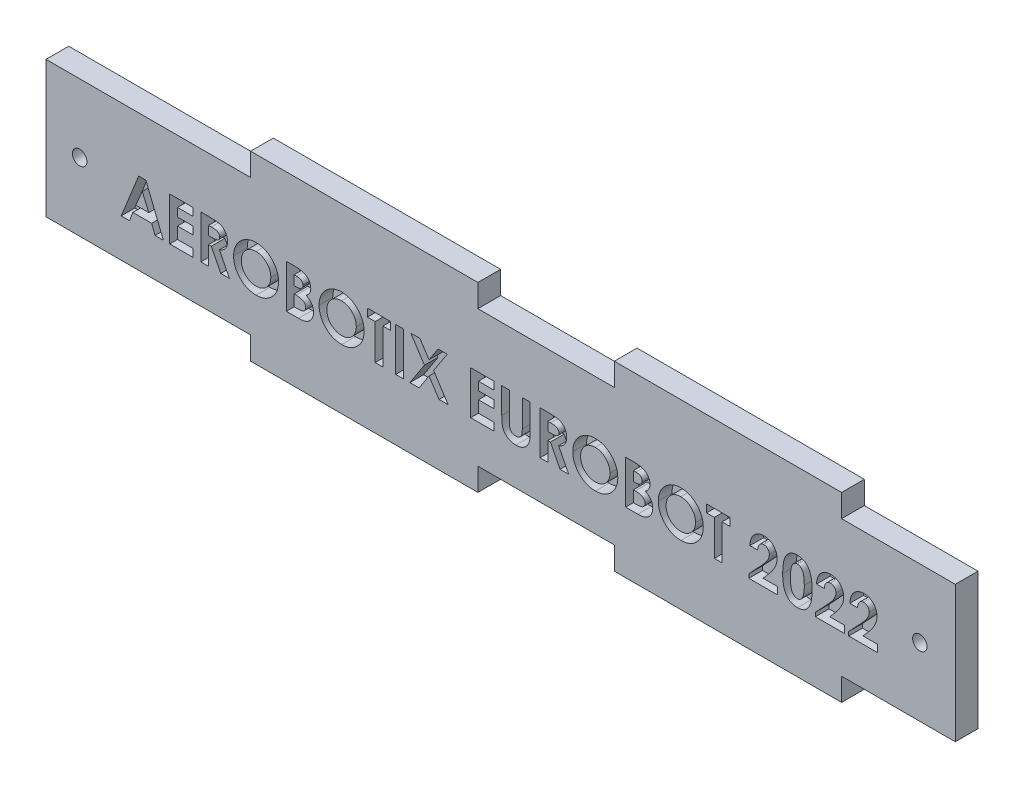
from build123d import *

# Parameters (mm, degrees)
ESQUISSE1_R             = 1.6
ESQUISSE1_R_2           = 1.589255924
BOSS_EXTRU_1_DEPTH      = 5
ESQUISSE2_W             = 1.709615384
ESQUISSE2_H             = 9.525
ENL_V_MAT_EXTRU_1_DEPTH = 3
ESQUISSE3_W             = 1.709615385
ESQUISSE3_H             = 9.525
ENL_V_MAT_EXTRU_2_DEPTH = 1


with BuildPart() as part:
    # Esquisse1 → Boss.-Extru.1 (new body)
    with BuildSketch(Plane.XY):
        Polygon((-155, 30), (-155, 35), (-105, 35), (-105, 30), (-75, 30), (-75, 35), (-25, 35), (-25, 30), (0, 30), (0, 0), (-25, 0), (-25, -5), (-75, -5), (-75, 0), (-105, 0), (-105, -5), (-155, -5), (-155, 0), (-200, 0), (-200, 30), align=None)
        with Locations((-192.6, 15)):
            Circle(ESQUISSE1_R, mode=Mode.SUBTRACT)
        with Locations((-7.8, 15)):
            Circle(ESQUISSE1_R_2, mode=Mode.SUBTRACT)
    extrude(amount=BOSS_EXTRU_1_DEPTH)

    # Esquisse2 → Enlèv. mat.-Extru.1 (cut)
    # profile 1 of 20: a face of its own
    with BuildSketch(Plane.XY.offset(5)):
        Polygon((-179.617322716, 17.962512132), (-178.031730769, 17.962512132), (-174.185096154, 8.437512132), (-176.011102764, 8.437512132), (-176.751427284, 10.391358286), (-180.901442308, 10.391358286), (-181.641766827, 8.437512132), (-183.465865385, 8.437512132), align=None)
        Polygon((-178.825480769, 15.407629319), (-180.252704327, 12.10097367), (-177.398257212, 12.10097367), align=None, mode=Mode.SUBTRACT)
    # profile 2 of 20: a face of its own
    with BuildSketch(Plane.XY.offset(5)):
        Polygon((-172.780769231, 17.962512132), (-167.651923077, 17.962512132), (-167.651923077, 16.252896747), (-171.071153846, 16.252896747), (-171.071153846, 14.421165978), (-167.651923077, 14.421165978), (-167.651923077, 12.711550593), (-171.071153846, 12.711550593), (-171.071153846, 10.147127516), (-167.651923077, 10.147127516), (-167.651923077, 8.437512132), (-172.780769231, 8.437512132), align=None)
    # profile 3 of 20: a face of its own
    with BuildSketch(Plane.XY.offset(5)):
        with BuildLine():
            Line((-165.942307692, 17.962512132), (-163.950300481, 17.962512132))
            add(Edge.make_bspline(
                [(-163.950300481, 17.962512132), (-163.81862941, 17.962044775), (-163.565388852, 17.961145916), (-163.2002298, 17.946964308), (-162.864780992, 17.927229436), (-162.558545767, 17.897113497), (-162.281655138, 17.857183403), (-162.033831595, 17.810112429), (-161.815082382, 17.756464963), (-161.623562651, 17.689615988), (-161.450725565, 17.614211357), (-161.289617371, 17.527570053), (-161.136683784, 17.430656855), (-160.992947, 17.320921715), (-160.857157911, 17.200338739), (-160.729060345, 17.06878655), (-160.610464437, 16.925149639), (-160.502104539, 16.77033561), (-160.403343215, 16.607474801), (-160.316058918, 16.436343604), (-160.245079182, 16.256823008), (-160.182360977, 16.071507474), (-160.137187086, 15.87774788), (-160.105769305, 15.677430508), (-160.082766435, 15.469850221), (-160.08144388, 15.32882939), (-160.080769231, 15.256893141)],
                knots=[0, 0, 0, 0, 1.749336639, 3.364467119, 4.854658419, 6.213483162, 7.451590619, 8.570285859, 9.5643256, 10.440900261, 11.26203566, 12.067320669, 12.869050712, 13.665104639, 14.467235401, 15.27997916, 16.102287765, 16.939272006, 17.78853747, 18.631303466, 19.488103222, 20.351255419, 21.228522269, 22.127379805, 23.044756219, 24, 24, 24, 24], degree=3))
            add(Edge.make_bspline(
                [(-160.080769231, 15.256893141), (-160.082521728, 15.181808223), (-160.085958055, 15.034580384), (-160.104467984, 14.818314696), (-160.138298318, 14.611406813), (-160.189539282, 14.414462535), (-160.248434114, 14.225030662), (-160.326749134, 14.04660633), (-160.415135374, 13.876594616), (-160.520109128, 13.717400399), (-160.635312696, 13.565487659), (-160.769292021, 13.426676735), (-160.913367302, 13.293507067), (-161.075637536, 13.17431995), (-161.248949698, 13.061056383), (-161.436747321, 12.958409427), (-161.637804772, 12.863798776), (-161.779158116, 12.811037341), (-161.851442308, 12.784056603)],
                knots=[0, 0, 0, 0, 1.099860209, 2.156625411, 3.176576793, 4.16617041, 5.135385252, 6.078461593, 7.016046972, 7.938469504, 8.868247731, 9.803980173, 10.76021508, 11.73834243, 12.748633912, 13.790971185, 14.870363756, 16, 16, 16, 16], degree=3))
            Line((-161.851442308, 12.784056603), (-159.653365385, 8.437512132))
            Line((-159.653365385, 8.437512132), (-161.553786058, 8.437512132))
            Line((-161.553786058, 8.437512132), (-163.652644231, 12.589435209))
            Line((-163.652644231, 12.589435209), (-164.232692308, 12.589435209))
            Line((-164.232692308, 12.589435209), (-164.232692308, 8.437512132))
            Line((-164.232692308, 8.437512132), (-165.942307692, 8.437512132))
            Line((-165.942307692, 8.437512132), (-165.942307692, 17.962512132))
        make_face()
        with BuildLine():
            Line((-164.232692308, 14.299050593), (-163.566781851, 14.299050593))
            add(Edge.make_bspline(
                [(-163.566781851, 14.299050593), (-163.485368762, 14.299967522), (-163.329480191, 14.301723244), (-163.105291951, 14.30986701), (-162.901675562, 14.329489461), (-162.717756629, 14.354281695), (-162.552609686, 14.38290791), (-162.407707787, 14.423931013), (-162.280818215, 14.467888307), (-162.173444616, 14.52251582), (-162.08170708, 14.584639151), (-162.002497589, 14.655212799), (-161.936979983, 14.736892811), (-161.883055651, 14.827459475), (-161.841108383, 14.927713833), (-161.810490092, 15.036555317), (-161.793378995, 15.155223773), (-161.791410305, 15.237121166), (-161.790384615, 15.279789776)],
                knots=[0, 0, 0, 0, 1.688639943, 3.233382647, 4.650958383, 5.928841754, 7.082724185, 8.122798841, 9.049171256, 9.863274652, 10.613301712, 11.341792392, 12.054588806, 12.776240173, 13.521029143, 14.301969904, 15.115324896, 16, 16, 16, 16], degree=3))
            add(Edge.make_bspline(
                [(-161.790384615, 15.279789776), (-161.792323775, 15.330269857), (-161.796132894, 15.429428622), (-161.833931189, 15.572182474), (-161.894097911, 15.70431093), (-161.976570007, 15.825217003), (-162.08043289, 15.931211613), (-162.199623743, 16.024646705), (-162.336714992, 16.098528186), (-162.463651173, 16.147259623), (-162.579133427, 16.176416145), (-162.683352517, 16.198143327), (-162.804038852, 16.213542005), (-162.941283541, 16.229875043), (-163.094736745, 16.240466192), (-163.265234875, 16.24819562), (-163.452288261, 16.251358108), (-163.582682237, 16.2523691), (-163.650736178, 16.252896747)],
                knots=[0, 0, 0, 0, 1.020303359, 2.004196876, 2.966617323, 3.9489082, 4.950758222, 5.960522915, 7.003732012, 8.091992268, 8.70421221, 9.413913587, 10.24622431, 11.166358409, 12.212345909, 13.359657661, 14.621978493, 16, 16, 16, 16], degree=3))
            Line((-163.650736178, 16.252896747), (-164.232692308, 16.252896747))
            Line((-164.232692308, 16.252896747), (-164.232692308, 14.299050593))
        make_face(mode=Mode.SUBTRACT)
    # profile 4 of 20: a face of its own
    with BuildSketch(Plane.XY.offset(5)):
        with BuildLine():
            add(Edge.make_bspline(
                [(-153.772746394, 18.206742901), (-153.607142596, 18.202455122), (-153.280203189, 18.193990075), (-152.799393302, 18.123427304), (-152.336044074, 18.008455385), (-151.890365031, 17.848636101), (-151.463472102, 17.639640735), (-151.053859492, 17.387394441), (-150.662994414, 17.087136223), (-150.294882141, 16.745870609), (-149.95468001, 16.374759156), (-149.659894665, 15.975191697), (-149.408512538, 15.557521428), (-149.200166358, 15.120629189), (-149.041471962, 14.661489293), (-148.93010954, 14.182442747), (-148.858564702, 13.683625834), (-148.850335944, 13.343999506), (-148.846153846, 13.171391339)],
                knots=[0, 0, 0, 0, 1.014329547, 2.002516266, 2.970391464, 3.935626869, 4.897733899, 5.877609409, 6.878433252, 7.912639331, 8.949961323, 9.958554974, 10.949718813, 11.932905612, 12.9188844, 13.919928257, 14.942845884, 16, 16, 16, 16], degree=3))
            add(Edge.make_bspline(
                [(-148.846153846, 13.171391339), (-148.8506076, 13.000728067), (-148.859383865, 12.664430615), (-148.927188767, 12.170210496), (-149.040426545, 11.696295536), (-149.19642936, 11.241613017), (-149.400996928, 10.808365266), (-149.64747683, 10.393786055), (-149.942373203, 10.00172278), (-150.274930018, 9.632385836), (-150.641046211, 9.297133308), (-151.028821379, 9.001692596), (-151.436465017, 8.751347287), (-151.863380464, 8.546212049), (-152.31048322, 8.387014146), (-152.776668886, 8.274688457), (-153.261908615, 8.206425868), (-153.591895162, 8.197706929), (-153.759390024, 8.193281363)],
                knots=[0, 0, 0, 0, 1.051557043, 2.072126891, 3.067553643, 4.050577992, 5.02905126, 6.015227836, 7.017913613, 8.04756643, 9.074058332, 10.072836633, 11.047628519, 12.017157415, 12.98668631, 13.966869689, 14.968021931, 16, 16, 16, 16], degree=3))
            add(Edge.make_bspline(
                [(-153.759390024, 8.193281363), (-153.934569566, 8.197251314), (-154.27877342, 8.205051726), (-154.782517302, 8.279230084), (-155.265147468, 8.390968603), (-155.722609547, 8.557732349), (-156.159562399, 8.766201053), (-156.572795603, 9.022942761), (-156.962170286, 9.327533188), (-157.32545293, 9.672171658), (-157.654587886, 10.049281736), (-157.945114044, 10.447665091), (-158.190179304, 10.864278425), (-158.38979263, 11.299316722), (-158.547159759, 11.750076325), (-158.658164388, 12.21930249), (-158.723737471, 12.705869842), (-158.732871421, 13.036356114), (-158.7375, 13.203828238)],
                knots=[0, 0, 0, 0, 1.067978421, 2.098431617, 3.099715153, 4.085208694, 5.062210972, 6.048429807, 7.046490867, 8.072918869, 9.098532598, 10.095778865, 11.076610158, 12.041847152, 13.011192615, 13.984257998, 14.978533688, 16, 16, 16, 16], degree=3))
            add(Edge.make_bspline(
                [(-158.7375, 13.203828238), (-158.736047285, 13.316494715), (-158.73316025, 13.540401054), (-158.698382872, 13.872218819), (-158.648313446, 14.197559947), (-158.574263141, 14.515127297), (-158.484310948, 14.827161161), (-158.367765174, 15.130757049), (-158.235104543, 15.4291582), (-158.080103086, 15.718840124), (-157.907756454, 15.997137504), (-157.719710934, 16.262737563), (-157.515493687, 16.512428808), (-157.295762566, 16.747852107), (-157.059760348, 16.967460006), (-156.810591397, 17.174361361), (-156.543423287, 17.363060134), (-156.264103489, 17.538164728), (-155.974206745, 17.696508776), (-155.674913197, 17.831286493), (-155.372388883, 17.948985578), (-155.062592487, 18.0418789), (-154.748844028, 18.117539539), (-154.427791739, 18.167575218), (-154.102336145, 18.202351633), (-153.882870372, 18.205275671), (-153.772746394, 18.206742901)],
                knots=[0, 0, 0, 0, 1.034744296, 2.056386356, 3.06226378, 4.057406941, 5.050368692, 6.043467995, 7.042652155, 8.049140477, 9.059438543, 10.048523776, 11.036952808, 12.020949711, 13.004946614, 13.997082645, 14.994316842, 16.007702937, 17.024872941, 18.026463647, 19.021641123, 20.005082605, 20.995858141, 21.984425357, 22.988620895, 24, 24, 24, 24], degree=3))
        make_face()
        with BuildLine():
            add(Edge.make_bspline(
                [(-153.799459135, 16.497127516), (-153.910910469, 16.494137027), (-154.130870805, 16.488234997), (-154.453512558, 16.443269514), (-154.763260036, 16.371454526), (-155.058396185, 16.267431393), (-155.340200151, 16.135036347), (-155.609171485, 15.97473199), (-155.86158549, 15.781008042), (-156.100807864, 15.564264675), (-156.316905913, 15.322762754), (-156.507835357, 15.063952374), (-156.667612549, 14.788265744), (-156.801426948, 14.498263928), (-156.902159534, 14.190685932), (-156.973908334, 13.867941047), (-157.019250897, 13.529473169), (-157.024966384, 13.298740056), (-157.027884615, 13.180931603)],
                knots=[0, 0, 0, 0, 1.033739768, 2.040188636, 3.016340934, 3.979330865, 4.937572243, 5.900995986, 6.878200029, 7.884839167, 8.891893314, 9.879764717, 10.863503415, 11.843163062, 12.837761627, 13.859916423, 14.907309254, 16, 16, 16, 16], degree=3))
            add(Edge.make_bspline(
                [(-157.027884615, 13.180931603), (-157.024015486, 13.050373336), (-157.016432634, 12.794500765), (-156.963078762, 12.421240752), (-156.871795597, 12.068733716), (-156.739984483, 11.738703716), (-156.57650412, 11.427486016), (-156.373487456, 11.138895032), (-156.134222398, 10.871202814), (-155.949894537, 10.714912947), (-155.856340144, 10.635589055)],
                knots=[0, 0, 0, 0, 1.078454662, 2.113592447, 3.107694534, 4.079536787, 5.043276885, 6.005368276, 6.987637804, 8, 8, 8, 8], degree=3))
            add(Edge.make_bspline(
                [(-155.856340144, 10.635589055), (-155.779701236, 10.57698761), (-155.628150108, 10.46110502), (-155.386241512, 10.312577708), (-155.137123292, 10.185274985), (-154.878915539, 10.082415892), (-154.612163574, 10.001508657), (-154.336903977, 9.944850651), (-154.053526768, 9.909292853), (-153.861893819, 9.905043022), (-153.765114183, 9.902896747)],
                knots=[0, 0, 0, 0, 1.023928204, 2.024787132, 3.009472467, 3.9914905, 4.972207045, 5.96565515, 6.972602802, 8, 8, 8, 8], degree=3))
            add(Edge.make_bspline(
                [(-153.765114183, 9.902896747), (-153.655579257, 9.905912593), (-153.440065845, 9.911846364), (-153.123430241, 9.956258297), (-152.820083716, 10.031419324), (-152.528143069, 10.134529929), (-152.248450125, 10.26858731), (-151.982371821, 10.433863804), (-151.729441648, 10.62833003), (-151.490524041, 10.847919711), (-151.272142055, 11.090372983), (-151.081611041, 11.350563831), (-150.916753733, 11.622759472), (-150.785722006, 11.910812422), (-150.681009704, 12.212003597), (-150.610124438, 12.527666908), (-150.564398832, 12.856501071), (-150.558681735, 13.080284339), (-150.555769231, 13.194287973)],
                knots=[0, 0, 0, 0, 1.026359118, 2.019393844, 2.989460624, 3.950973911, 4.916101784, 5.890408035, 6.881132271, 7.902007068, 8.92769091, 9.933912415, 10.920395702, 11.90457117, 12.894218921, 13.903490204, 14.931958862, 16, 16, 16, 16], degree=3))
            add(Edge.make_bspline(
                [(-150.555769231, 13.194287973), (-150.558782509, 13.307636055), (-150.564713686, 13.530744468), (-150.609203787, 13.8587332), (-150.683888162, 14.17300295), (-150.787308398, 14.474066953), (-150.919370561, 14.762220365), (-151.082678824, 15.036449867), (-151.276660158, 15.296490346), (-151.496850093, 15.540569726), (-151.736513305, 15.764863042), (-151.99381571, 15.959508868), (-152.261557698, 16.128649902), (-152.545882576, 16.261148158), (-152.840973296, 16.366709238), (-153.148630516, 16.444445931), (-153.470019507, 16.487919113), (-153.688667083, 16.494030688), (-153.799459135, 16.497127516)],
                knots=[0, 0, 0, 0, 1.055025985, 2.07665775, 3.074803781, 4.057872707, 5.035505728, 6.020516407, 7.023567878, 8.050795229, 9.077271434, 10.074415901, 11.050397877, 12.019801805, 12.988065821, 13.964604439, 14.968634123, 16, 16, 16, 16], degree=3))
        make_face(mode=Mode.SUBTRACT)
    # profile 5 of 20: a face of its own
    with BuildSketch(Plane.XY.offset(5)):
        with BuildLine():
            Line((-147.136538462, 8.437512132), (-147.136538462, 17.962512132))
            Line((-147.136538462, 17.962512132), (-145.610096154, 17.962512132))
            add(Edge.make_bspline(
                [(-145.610096154, 17.962512132), (-145.503235648, 17.962524327), (-145.296462595, 17.962547925), (-144.998143042, 17.952071922), (-144.721476851, 17.938520038), (-144.46734448, 17.923358631), (-144.235313378, 17.897232499), (-144.025736388, 17.869698408), (-143.838194772, 17.836493993), (-143.722247982, 17.806708603), (-143.667698317, 17.792695425)],
                knots=[0, 0, 0, 0, 1.311965854, 2.538629056, 3.664479157, 4.713267157, 5.663616078, 6.530575999, 7.308677837, 8, 8, 8, 8], degree=3))
            add(Edge.make_bspline(
                [(-143.667698317, 17.792695425), (-143.59606907, 17.772929588), (-143.455509491, 17.73414267), (-143.254183319, 17.655810814), (-143.063197361, 17.568739401), (-142.882784806, 17.469407205), (-142.714053459, 17.356615006), (-142.557644557, 17.229467652), (-142.410184746, 17.093068833), (-142.276909988, 16.943617151), (-142.156451566, 16.785693766), (-142.051794794, 16.619340056), (-141.960861473, 16.447099678), (-141.888090998, 16.266805103), (-141.833259812, 16.079286636), (-141.793156512, 15.885345008), (-141.767164142, 15.684366542), (-141.764708204, 15.547634322), (-141.763461538, 15.478227276)],
                knots=[0, 0, 0, 0, 1.099996261, 2.158545794, 3.195537121, 4.207578794, 5.205712374, 6.197378256, 7.190519799, 8.17788031, 9.159561366, 10.129234751, 11.085776129, 12.040971148, 13.00380137, 13.975669004, 14.972423361, 16, 16, 16, 16], degree=3))
            add(Edge.make_bspline(
                [(-141.763461538, 15.478227276), (-141.7667212, 15.38905744), (-141.773137442, 15.213537574), (-141.814124834, 14.955730646), (-141.890982582, 14.712066044), (-141.991549075, 14.478053121), (-142.128288064, 14.254564746), (-142.301920135, 14.041707183), (-142.509633016, 13.832926228), (-142.668960263, 13.707776128), (-142.751832933, 13.642680401)],
                knots=[0, 0, 0, 0, 0.986156485, 1.941127874, 2.875419072, 3.804401753, 4.751181392, 5.761612777, 6.835722519, 8, 8, 8, 8], degree=3))
            add(Edge.make_bspline(
                [(-142.751832933, 13.642680401), (-142.684676897, 13.608397827), (-142.55300249, 13.541179184), (-142.366063517, 13.430691802), (-142.192978433, 13.313174458), (-142.032971178, 13.190991648), (-141.889398088, 13.058963867), (-141.756330788, 12.924698737), (-141.640334128, 12.780503423), (-141.536606419, 12.631517321), (-141.44644798, 12.475583096), (-141.367929922, 12.312964085), (-141.301608534, 12.143104746), (-141.245445868, 11.966869526), (-141.203559737, 11.783652258), (-141.176249088, 11.593387416), (-141.155338349, 11.396723899), (-141.15371169, 11.262761623), (-141.152884615, 11.19464855)],
                knots=[0, 0, 0, 0, 1.164658916, 2.283573913, 3.35186032, 4.395461096, 5.390182219, 6.362969632, 7.312859996, 8.245001507, 9.165155236, 10.092416118, 11.032087915, 11.979892451, 12.947605196, 13.931445124, 14.948243989, 16, 16, 16, 16], degree=3))
            add(Edge.make_bspline(
                [(-141.152884615, 11.19464855), (-141.158251774, 11.064556475), (-141.168843841, 10.807820287), (-141.246287862, 10.430872599), (-141.380551188, 10.073492002), (-141.560839149, 9.737098878), (-141.782988604, 9.431431258), (-142.038396772, 9.163669076), (-142.324492278, 8.937014334), (-142.588449962, 8.784039966), (-142.816752572, 8.68137986), (-143.005851358, 8.617908909), (-143.208939446, 8.559109516), (-143.429736922, 8.517819368), (-143.664241029, 8.480026084), (-143.914738197, 8.456691727), (-144.18076025, 8.440878609), (-144.363475696, 8.438656978), (-144.457632212, 8.437512132)],
                knots=[0, 0, 0, 0, 1.284142165, 2.534249414, 3.780121997, 5.041676246, 6.291546858, 7.49970053, 8.684500223, 9.883330709, 10.50184324, 11.153274765, 11.851151195, 12.587658647, 13.369265475, 14.195992086, 15.070362669, 16, 16, 16, 16], degree=3))
            Line((-144.457632212, 8.437512132), (-147.136538462, 8.437512132))
        make_face()
        with BuildLine():
            Line((-145.426923077, 16.252896747), (-145.426923077, 14.176935209))
            Line((-145.426923077, 14.176935209), (-144.97280649, 14.176935209))
            add(Edge.make_bspline(
                [(-144.97280649, 14.176935209), (-144.911087966, 14.177473418), (-144.791944091, 14.178512397), (-144.6198534, 14.191894095), (-144.459836849, 14.214724102), (-144.312501347, 14.246577705), (-144.176474409, 14.287027136), (-144.052625015, 14.335696513), (-143.941497708, 14.395078444), (-143.81239348, 14.483530449), (-143.675921, 14.613691536), (-143.555785811, 14.801736193), (-143.485026987, 15.017986834), (-143.477146363, 15.17050353), (-143.473076923, 15.24926093)],
                knots=[0, 0, 0, 0, 1.065314748, 2.056525647, 2.977365736, 3.853934255, 4.656397591, 5.425096493, 6.14721249, 6.826394842, 8.123232004, 9.372140726, 10.643011755, 12, 12, 12, 12], degree=3))
            add(Edge.make_bspline(
                [(-143.473076923, 15.24926093), (-143.47633322, 15.32303032), (-143.482629139, 15.465660472), (-143.553874177, 15.665925908), (-143.664531806, 15.843402071), (-143.795178691, 15.964869991), (-143.918208119, 16.047828999), (-144.023553466, 16.102453973), (-144.139177894, 16.151353692), (-144.26731977, 16.188743608), (-144.407247331, 16.216799685), (-144.558280873, 16.237403514), (-144.72068098, 16.251427356), (-144.832851079, 16.252396444), (-144.890760216, 16.252896747)],
                knots=[0, 0, 0, 0, 1.347982417, 2.606269829, 3.849316587, 5.153353503, 5.842674298, 6.568177932, 7.326619318, 8.142485038, 9.012069166, 9.942760135, 10.937925643, 12, 12, 12, 12], degree=3))
            Line((-144.890760216, 16.252896747), (-145.426923077, 16.252896747))
        make_face(mode=Mode.SUBTRACT)
        with BuildLine():
            Line((-145.426923077, 12.589435209), (-145.426923077, 10.147127516))
            Line((-145.426923077, 10.147127516), (-144.934645433, 10.147127516))
            add(Edge.make_bspline(
                [(-144.934645433, 10.147127516), (-144.837321516, 10.147683524), (-144.650204141, 10.148752519), (-144.382158832, 10.161668516), (-144.138438636, 10.184947325), (-143.919689318, 10.214009043), (-143.725575822, 10.253383124), (-143.556754298, 10.303442223), (-143.410909578, 10.358515951), (-143.288916155, 10.426538544), (-143.189254517, 10.505699974), (-143.099320337, 10.586604857), (-143.025993611, 10.679936283), (-142.967976137, 10.781687793), (-142.917762116, 10.889331806), (-142.887476564, 11.007071781), (-142.864418208, 11.131418188), (-142.863149245, 11.217425909), (-142.8625, 11.261430401)],
                knots=[0, 0, 0, 0, 1.753078804, 3.370512758, 4.83203934, 6.162291463, 7.344201807, 8.395507345, 9.331626367, 10.147333109, 10.898971645, 11.62040215, 12.321813352, 13.025280112, 13.727906689, 14.453419512, 15.208716525, 16, 16, 16, 16], degree=3))
            add(Edge.make_bspline(
                [(-142.8625, 11.261430401), (-142.863931771, 11.311750229), (-142.866720477, 11.409759718), (-142.889495868, 11.553011047), (-142.930886193, 11.686745666), (-142.983019327, 11.814383351), (-143.055565352, 11.931354229), (-143.141783825, 12.041706218), (-143.245957749, 12.141702459), (-143.363107405, 12.237391097), (-143.49975088, 12.321171685), (-143.655952284, 12.393866184), (-143.832560186, 12.454577953), (-144.03012165, 12.502916704), (-144.247770581, 12.543941133), (-144.487095577, 12.568437246), (-144.746103456, 12.586656082), (-144.925703734, 12.588487784), (-145.01859976, 12.589435209)],
                knots=[0, 0, 0, 0, 0.845221588, 1.646264278, 2.427170338, 3.19324141, 3.95557735, 4.731569926, 5.540061037, 6.376114724, 7.268642756, 8.224665384, 9.265483498, 10.400594375, 11.639216012, 12.983232105, 14.439614077, 16, 16, 16, 16], degree=3))
            Line((-145.01859976, 12.589435209), (-145.426923077, 12.589435209))
        make_face(mode=Mode.SUBTRACT)
    # profile 6 of 20: a face of its own
    with BuildSketch(Plane.XY.offset(5)):
        with BuildLine():
            add(Edge.make_bspline(
                [(-134.966977163, 18.206742901), (-134.801373365, 18.202455122), (-134.474433958, 18.193990075), (-133.993624071, 18.123427304), (-133.530274843, 18.008455385), (-133.0845958, 17.848636101), (-132.657702871, 17.639640735), (-132.248090261, 17.387394441), (-131.857225184, 17.087136223), (-131.489112911, 16.745870609), (-131.14891078, 16.374759156), (-130.854125435, 15.975191697), (-130.602743307, 15.557521428), (-130.394397127, 15.120629189), (-130.235702731, 14.661489293), (-130.124340309, 14.182442747), (-130.052795471, 13.683625834), (-130.044566714, 13.343999506), (-130.040384615, 13.171391339)],
                knots=[0, 0, 0, 0, 1.014329547, 2.002516266, 2.970391464, 3.935626869, 4.897733899, 5.877609409, 6.878433252, 7.912639331, 8.949961323, 9.958554974, 10.949718813, 11.932905612, 12.9188844, 13.919928257, 14.942845884, 16, 16, 16, 16], degree=3))
            add(Edge.make_bspline(
                [(-130.040384615, 13.171391339), (-130.044838369, 13.000728067), (-130.053614634, 12.664430615), (-130.121419536, 12.170210496), (-130.234657315, 11.696295536), (-130.390660129, 11.241613017), (-130.595227697, 10.808365266), (-130.841707599, 10.393786055), (-131.136603973, 10.00172278), (-131.469160787, 9.632385836), (-131.83527698, 9.297133308), (-132.223052148, 9.001692596), (-132.630695786, 8.751347287), (-133.057611233, 8.546212049), (-133.504713989, 8.387014146), (-133.970899655, 8.274688457), (-134.456139384, 8.206425868), (-134.786125932, 8.197706929), (-134.953620793, 8.193281363)],
                knots=[0, 0, 0, 0, 1.051557043, 2.072126891, 3.067553643, 4.050577992, 5.02905126, 6.015227836, 7.017913613, 8.04756643, 9.074058332, 10.072836633, 11.047628519, 12.017157415, 12.98668631, 13.966869689, 14.968021931, 16, 16, 16, 16], degree=3))
            add(Edge.make_bspline(
                [(-134.953620793, 8.193281363), (-135.128800335, 8.197251314), (-135.47300419, 8.205051726), (-135.976748072, 8.279230084), (-136.459378238, 8.390968603), (-136.916840316, 8.557732349), (-137.353793168, 8.766201053), (-137.767026372, 9.022942761), (-138.156401055, 9.327533188), (-138.519683699, 9.672171658), (-138.848818655, 10.049281736), (-139.139344813, 10.447665091), (-139.384410073, 10.864278425), (-139.5840234, 11.299316722), (-139.741390528, 11.750076325), (-139.852395157, 12.21930249), (-139.91796824, 12.705869842), (-139.92710219, 13.036356114), (-139.931730769, 13.203828238)],
                knots=[0, 0, 0, 0, 1.067978421, 2.098431617, 3.099715153, 4.085208694, 5.062210972, 6.048429807, 7.046490867, 8.072918869, 9.098532598, 10.095778865, 11.076610158, 12.041847152, 13.011192615, 13.984257998, 14.978533688, 16, 16, 16, 16], degree=3))
            add(Edge.make_bspline(
                [(-139.931730769, 13.203828238), (-139.930278054, 13.316494715), (-139.927391019, 13.540401054), (-139.892613641, 13.872218819), (-139.842544216, 14.197559947), (-139.768493911, 14.515127297), (-139.678541717, 14.827161161), (-139.561995943, 15.130757049), (-139.429335312, 15.4291582), (-139.274333856, 15.718840124), (-139.101987223, 15.997137504), (-138.913941703, 16.262737563), (-138.709724456, 16.512428808), (-138.489993336, 16.747852107), (-138.253991117, 16.967460006), (-138.004822166, 17.174361361), (-137.737654056, 17.363060134), (-137.458334258, 17.538164728), (-137.168437514, 17.696508776), (-136.869143966, 17.831286493), (-136.566619652, 17.948985578), (-136.256823256, 18.0418789), (-135.943074797, 18.117539539), (-135.622022508, 18.167575218), (-135.296566914, 18.202351633), (-135.077101141, 18.205275671), (-134.966977163, 18.206742901)],
                knots=[0, 0, 0, 0, 1.034744296, 2.056386356, 3.06226378, 4.057406941, 5.050368692, 6.043467995, 7.042652155, 8.049140477, 9.059438543, 10.048523776, 11.036952808, 12.020949711, 13.004946614, 13.997082645, 14.994316842, 16.007702937, 17.024872941, 18.026463647, 19.021641123, 20.005082605, 20.995858141, 21.984425357, 22.988620895, 24, 24, 24, 24], degree=3))
        make_face()
        with BuildLine():
            add(Edge.make_bspline(
                [(-134.993689904, 16.497127516), (-135.105141238, 16.494137027), (-135.325101574, 16.488234997), (-135.647743328, 16.443269514), (-135.957490805, 16.371454526), (-136.252626954, 16.267431393), (-136.53443092, 16.135036347), (-136.803402254, 15.97473199), (-137.05581626, 15.781008042), (-137.295038633, 15.564264675), (-137.511136682, 15.322762754), (-137.702066126, 15.063952374), (-137.861843318, 14.788265744), (-137.995657718, 14.498263928), (-138.096390303, 14.190685932), (-138.168139103, 13.867941047), (-138.213481667, 13.529473169), (-138.219197153, 13.298740056), (-138.222115385, 13.180931603)],
                knots=[0, 0, 0, 0, 1.033739768, 2.040188636, 3.016340934, 3.979330865, 4.937572243, 5.900995986, 6.878200029, 7.884839167, 8.891893314, 9.879764717, 10.863503415, 11.843163062, 12.837761627, 13.859916423, 14.907309254, 16, 16, 16, 16], degree=3))
            add(Edge.make_bspline(
                [(-138.222115385, 13.180931603), (-138.218246255, 13.050373336), (-138.210663403, 12.794500765), (-138.157309531, 12.421240752), (-138.066026367, 12.068733716), (-137.934215252, 11.738703716), (-137.77073489, 11.427486016), (-137.567718225, 11.138895032), (-137.328453168, 10.871202814), (-137.144125306, 10.714912947), (-137.050570913, 10.635589055)],
                knots=[0, 0, 0, 0, 1.078454662, 2.113592447, 3.107694534, 4.079536787, 5.043276885, 6.005368276, 6.987637804, 8, 8, 8, 8], degree=3))
            add(Edge.make_bspline(
                [(-137.050570913, 10.635589055), (-136.973932005, 10.57698761), (-136.822380877, 10.46110502), (-136.580472281, 10.312577708), (-136.331354061, 10.185274985), (-136.073146308, 10.082415892), (-135.806394343, 10.001508657), (-135.531134746, 9.944850651), (-135.247757537, 9.909292853), (-135.056124588, 9.905043022), (-134.959344952, 9.902896747)],
                knots=[0, 0, 0, 0, 1.023928204, 2.024787132, 3.009472467, 3.9914905, 4.972207045, 5.96565515, 6.972602802, 8, 8, 8, 8], degree=3))
            add(Edge.make_bspline(
                [(-134.959344952, 9.902896747), (-134.849810026, 9.905912593), (-134.634296614, 9.911846364), (-134.317661011, 9.956258297), (-134.014314486, 10.031419324), (-133.722373838, 10.134529929), (-133.442680894, 10.26858731), (-133.17660259, 10.433863804), (-132.923672418, 10.62833003), (-132.684754811, 10.847919711), (-132.466372824, 11.090372983), (-132.27584181, 11.350563831), (-132.110984502, 11.622759472), (-131.979952775, 11.910812422), (-131.875240473, 12.212003597), (-131.804355207, 12.527666908), (-131.758629601, 12.856501071), (-131.752912505, 13.080284339), (-131.75, 13.194287973)],
                knots=[0, 0, 0, 0, 1.026359118, 2.019393844, 2.989460624, 3.950973911, 4.916101784, 5.890408035, 6.881132271, 7.902007068, 8.92769091, 9.933912415, 10.920395702, 11.90457117, 12.894218921, 13.903490204, 14.931958862, 16, 16, 16, 16], degree=3))
            add(Edge.make_bspline(
                [(-131.75, 13.194287973), (-131.753013278, 13.307636055), (-131.758944455, 13.530744468), (-131.803434557, 13.8587332), (-131.878118932, 14.17300295), (-131.981539167, 14.474066953), (-132.113601331, 14.762220365), (-132.276909593, 15.036449867), (-132.470890927, 15.296490346), (-132.691080863, 15.540569726), (-132.930744075, 15.764863042), (-133.188046479, 15.959508868), (-133.455788467, 16.128649902), (-133.740113345, 16.261148158), (-134.035204065, 16.366709238), (-134.342861285, 16.444445931), (-134.664250277, 16.487919113), (-134.882897853, 16.494030688), (-134.993689904, 16.497127516)],
                knots=[0, 0, 0, 0, 1.055025985, 2.07665775, 3.074803781, 4.057872707, 5.035505728, 6.020516407, 7.023567878, 8.050795229, 9.077271434, 10.074415901, 11.050397877, 12.019801805, 12.988065821, 13.964604439, 14.968634123, 16, 16, 16, 16], degree=3))
        make_face(mode=Mode.SUBTRACT)
    # profile 7 of 20: a face of its own
    with BuildSketch(Plane.XY.offset(5)):
        Polygon((-129.307692308, 17.962512132), (-124.178846154, 17.962512132), (-124.178846154, 16.252896747), (-125.888461538, 16.252896747), (-125.888461538, 8.437512132), (-127.598076923, 8.437512132), (-127.598076923, 16.252896747), (-129.307692308, 16.252896747), align=None)
    # profile 8 of 20: a face of its own
    with BuildSketch(Plane.XY.offset(5)):
        with Locations((-122.225, 13.200012132)):
            Rectangle(ESQUISSE2_W, ESQUISSE2_H)
    # profile 9 of 20: a face of its own
    with BuildSketch(Plane.XY.offset(5)):
        Polygon((-119.754071514, 17.962512132), (-117.739167668, 17.962512132), (-115.74906851, 14.903903358), (-113.755153245, 17.962512132), (-111.738341346, 17.962512132), (-114.741616587, 13.356472468), (-111.539903846, 8.437512132), (-113.554807692, 8.437512132), (-115.74906851, 11.810949632), (-117.949053486, 8.437512132), (-119.965865385, 8.437512132), (-116.756520433, 13.358380521), align=None)
    # profile 10 of 20: a face of its own
    with BuildSketch(Plane.XY.offset(5)):
        Polygon((-106.594230769, 17.962512132), (-101.465384615, 17.962512132), (-101.465384615, 16.252896747), (-104.884615385, 16.252896747), (-104.884615385, 14.421165978), (-101.465384615, 14.421165978), (-101.465384615, 12.711550593), (-104.884615385, 12.711550593), (-104.884615385, 10.147127516), (-101.465384615, 10.147127516), (-101.465384615, 8.437512132), (-106.594230769, 8.437512132), align=None)
    # profile 11 of 20: a face of its own
    with BuildSketch(Plane.XY.offset(5)):
        with BuildLine():
            Line((-99.755769231, 17.962512132), (-98.046153846, 17.962512132))
            Line((-98.046153846, 17.962512132), (-98.046153846, 11.765156363))
            add(Edge.make_bspline(
                [(-98.046153846, 11.765156363), (-98.046060886, 11.700904866), (-98.045881334, 11.576803764), (-98.036892859, 11.398759314), (-98.028667785, 11.235099186), (-98.013827417, 11.086002552), (-97.991903107, 10.951405636), (-97.970673221, 10.830443832), (-97.94194067, 10.725282827), (-97.898760238, 10.605582072), (-97.832233369, 10.471091735), (-97.723532155, 10.33092282), (-97.598100253, 10.202998341), (-97.447762894, 10.096518851), (-97.278796998, 10.010386542), (-97.092130958, 9.946572032), (-96.888027905, 9.911099638), (-96.746901841, 9.905684127), (-96.674263822, 9.902896747)],
                knots=[0, 0, 0, 0, 1.155499968, 2.231836252, 3.205919964, 4.102923608, 4.924856345, 5.658536265, 6.31071849, 6.882491295, 7.94666036, 8.992281882, 10.060072772, 11.158554251, 12.289267114, 13.461410017, 14.693379945, 16, 16, 16, 16], degree=3))
            add(Edge.make_bspline(
                [(-96.674263822, 9.902896747), (-96.597094891, 9.905148592), (-96.446628541, 9.909539309), (-96.23020665, 9.952638949), (-96.029690541, 10.021268336), (-95.849325823, 10.119219962), (-95.689291989, 10.236632152), (-95.553826701, 10.370518843), (-95.446917994, 10.52114707), (-95.377238876, 10.66011308), (-95.338117483, 10.788019191), (-95.30879405, 10.902298448), (-95.287296729, 11.037136658), (-95.267793654, 11.190428034), (-95.256073808, 11.363760378), (-95.243365545, 11.555739728), (-95.238707849, 11.76767966), (-95.237913979, 11.915257412), (-95.2375, 11.992214656)],
                knots=[0, 0, 0, 0, 1.261321664, 2.459363699, 3.594844139, 4.716940403, 5.803436589, 6.833651888, 7.818396249, 8.814403945, 9.360733334, 10.004355033, 10.743453831, 11.592799886, 12.532235708, 13.585170094, 14.740740724, 16, 16, 16, 16], degree=3))
            Line((-95.2375, 11.992214656), (-95.2375, 17.962512132))
            Line((-95.2375, 17.962512132), (-93.527884615, 17.962512132))
            Line((-93.527884615, 17.962512132), (-93.527884615, 12.280330641))
            add(Edge.make_bspline(
                [(-93.527884615, 12.280330641), (-93.528122027, 12.165209916), (-93.528578545, 11.943843988), (-93.535589293, 11.625725572), (-93.550513908, 11.335175428), (-93.563048863, 11.072108657), (-93.587308294, 10.836879653), (-93.612580929, 10.628483923), (-93.644793078, 10.447659973), (-93.692722818, 10.24181388), (-93.77543536, 10.004789643), (-93.908778821, 9.73186651), (-94.078049714, 9.46465823), (-94.27811945, 9.20610428), (-94.504016484, 8.965915992), (-94.750732193, 8.755061765), (-95.01434688, 8.576701827), (-95.297615127, 8.435197292), (-95.600295861, 8.324834422), (-95.92538388, 8.250676132), (-96.2726575, 8.20057386), (-96.512525953, 8.195760921), (-96.636102764, 8.193281363)],
                knots=[0, 0, 0, 0, 1.170808336, 2.251350247, 3.235597562, 4.129743112, 4.929140599, 5.639994148, 6.264258765, 6.79612947, 7.788252245, 8.809469599, 9.879094798, 10.999557536, 12.129761673, 13.226370002, 14.293821979, 15.358369427, 16.438775801, 17.562147481, 18.744053101, 20, 20, 20, 20], degree=3))
            add(Edge.make_bspline(
                [(-96.636102764, 8.193281363), (-96.718209656, 8.194664345), (-96.880204869, 8.19739294), (-97.118447249, 8.221452024), (-97.348755308, 8.256906068), (-97.570696301, 8.308629866), (-97.785040543, 8.375447353), (-97.991731086, 8.457695026), (-98.18999982, 8.554914118), (-98.378737261, 8.666210424), (-98.55771115, 8.786558219), (-98.721284047, 8.919968817), (-98.875084878, 9.056575999), (-99.014670401, 9.202128775), (-99.141089029, 9.35509909), (-99.254080401, 9.515833624), (-99.353476651, 9.684318101), (-99.441778036, 9.863589443), (-99.517355403, 10.062759365), (-99.581069963, 10.288912424), (-99.636732501, 10.545593343), (-99.678097616, 10.83338041), (-99.715599472, 11.151325111), (-99.739336079, 11.500255741), (-99.751753766, 11.88018231), (-99.754396921, 12.143577525), (-99.755769231, 12.280330641)],
                knots=[0, 0, 0, 0, 1.001158378, 1.975264943, 2.917723546, 3.841610987, 4.75185031, 5.653588123, 6.552117133, 7.442167995, 8.324307438, 9.179605724, 10.014504199, 10.831958861, 11.636465792, 12.43274043, 13.225645099, 14.020104002, 14.867201867, 15.819789774, 16.883317127, 18.068162734, 19.364263498, 20.787406516, 22.332041935, 24, 24, 24, 24], degree=3))
            Line((-99.755769231, 12.280330641), (-99.755769231, 17.962512132))
        make_face()
    # profile 12 of 20: a face of its own
    with BuildSketch(Plane.XY.offset(5)):
        with BuildLine():
            Line((-91.329807692, 17.962512132), (-89.337800481, 17.962512132))
            add(Edge.make_bspline(
                [(-89.337800481, 17.962512132), (-89.20612941, 17.962044775), (-88.952888852, 17.961145916), (-88.5877298, 17.946964308), (-88.252280992, 17.927229436), (-87.946045767, 17.897113497), (-87.669155138, 17.857183403), (-87.421331595, 17.810112429), (-87.202582382, 17.756464963), (-87.011062651, 17.689615988), (-86.838225565, 17.614211357), (-86.677117371, 17.527570053), (-86.524183784, 17.430656855), (-86.380447, 17.320921715), (-86.244657911, 17.200338739), (-86.116560345, 17.06878655), (-85.997964437, 16.925149639), (-85.889604539, 16.77033561), (-85.790843215, 16.607474801), (-85.703558918, 16.436343604), (-85.632579182, 16.256823008), (-85.569860977, 16.071507474), (-85.524687086, 15.87774788), (-85.493269305, 15.677430508), (-85.470266435, 15.469850221), (-85.46894388, 15.32882939), (-85.468269231, 15.256893141)],
                knots=[0, 0, 0, 0, 1.749336639, 3.364467119, 4.854658419, 6.213483162, 7.451590619, 8.570285859, 9.5643256, 10.440900261, 11.26203566, 12.067320669, 12.869050712, 13.665104639, 14.467235401, 15.27997916, 16.102287765, 16.939272006, 17.78853747, 18.631303466, 19.488103222, 20.351255419, 21.228522269, 22.127379805, 23.044756219, 24, 24, 24, 24], degree=3))
            add(Edge.make_bspline(
                [(-85.468269231, 15.256893141), (-85.470021728, 15.181808223), (-85.473458055, 15.034580384), (-85.491967984, 14.818314696), (-85.525798318, 14.611406813), (-85.577039282, 14.414462535), (-85.635934114, 14.225030662), (-85.714249134, 14.04660633), (-85.802635374, 13.876594616), (-85.907609128, 13.717400399), (-86.022812696, 13.565487659), (-86.156792021, 13.426676735), (-86.300867302, 13.293507067), (-86.463137536, 13.17431995), (-86.636449698, 13.061056383), (-86.824247321, 12.958409427), (-87.025304772, 12.863798776), (-87.166658116, 12.811037341), (-87.238942308, 12.784056603)],
                knots=[0, 0, 0, 0, 1.099860209, 2.156625411, 3.176576793, 4.16617041, 5.135385252, 6.078461593, 7.016046972, 7.938469504, 8.868247731, 9.803980173, 10.76021508, 11.73834243, 12.748633912, 13.790971185, 14.870363756, 16, 16, 16, 16], degree=3))
            Line((-87.238942308, 12.784056603), (-85.040865385, 8.437512132))
            Line((-85.040865385, 8.437512132), (-86.941286058, 8.437512132))
            Line((-86.941286058, 8.437512132), (-89.040144231, 12.589435209))
            Line((-89.040144231, 12.589435209), (-89.620192308, 12.589435209))
            Line((-89.620192308, 12.589435209), (-89.620192308, 8.437512132))
            Line((-89.620192308, 8.437512132), (-91.329807692, 8.437512132))
            Line((-91.329807692, 8.437512132), (-91.329807692, 17.962512132))
        make_face()
        with BuildLine():
            Line((-89.620192308, 14.299050593), (-88.954281851, 14.299050593))
            add(Edge.make_bspline(
                [(-88.954281851, 14.299050593), (-88.872868762, 14.299967522), (-88.716980191, 14.301723244), (-88.492791951, 14.30986701), (-88.289175562, 14.329489461), (-88.105256629, 14.354281695), (-87.940109686, 14.38290791), (-87.795207787, 14.423931013), (-87.668318215, 14.467888307), (-87.560944616, 14.52251582), (-87.46920708, 14.584639151), (-87.389997589, 14.655212799), (-87.324479983, 14.736892811), (-87.270555651, 14.827459475), (-87.228608383, 14.927713833), (-87.197990092, 15.036555317), (-87.180878995, 15.155223773), (-87.178910305, 15.237121166), (-87.177884615, 15.279789776)],
                knots=[0, 0, 0, 0, 1.688639943, 3.233382647, 4.650958383, 5.928841754, 7.082724185, 8.122798841, 9.049171256, 9.863274652, 10.613301712, 11.341792392, 12.054588806, 12.776240173, 13.521029143, 14.301969904, 15.115324896, 16, 16, 16, 16], degree=3))
            add(Edge.make_bspline(
                [(-87.177884615, 15.279789776), (-87.179823775, 15.330269857), (-87.183632894, 15.429428622), (-87.221431189, 15.572182474), (-87.281597911, 15.70431093), (-87.364070007, 15.825217003), (-87.46793289, 15.931211613), (-87.587123743, 16.024646705), (-87.724214992, 16.098528186), (-87.851151173, 16.147259623), (-87.966633427, 16.176416145), (-88.070852517, 16.198143327), (-88.191538852, 16.213542005), (-88.328783541, 16.229875043), (-88.482236745, 16.240466192), (-88.652734875, 16.24819562), (-88.839788261, 16.251358108), (-88.970182237, 16.2523691), (-89.038236178, 16.252896747)],
                knots=[0, 0, 0, 0, 1.020303359, 2.004196876, 2.966617323, 3.9489082, 4.950758222, 5.960522915, 7.003732012, 8.091992268, 8.70421221, 9.413913587, 10.24622431, 11.166358409, 12.212345909, 13.359657661, 14.621978493, 16, 16, 16, 16], degree=3))
            Line((-89.038236178, 16.252896747), (-89.620192308, 16.252896747))
            Line((-89.620192308, 16.252896747), (-89.620192308, 14.299050593))
        make_face(mode=Mode.SUBTRACT)
    # profile 13 of 20: a face of its own
    with BuildSketch(Plane.XY.offset(5)):
        with BuildLine():
            add(Edge.make_bspline(
                [(-79.160246394, 18.206742901), (-78.994642596, 18.202455122), (-78.667703189, 18.193990075), (-78.186893302, 18.123427304), (-77.723544074, 18.008455385), (-77.277865031, 17.848636101), (-76.850972102, 17.639640735), (-76.441359492, 17.387394441), (-76.050494414, 17.087136223), (-75.682382141, 16.745870609), (-75.34218001, 16.374759156), (-75.047394665, 15.975191697), (-74.796012538, 15.557521428), (-74.587666358, 15.120629189), (-74.428971962, 14.661489293), (-74.31760954, 14.182442747), (-74.246064702, 13.683625834), (-74.237835944, 13.343999506), (-74.233653846, 13.171391339)],
                knots=[0, 0, 0, 0, 1.014329547, 2.002516266, 2.970391464, 3.935626869, 4.897733899, 5.877609409, 6.878433252, 7.912639331, 8.949961323, 9.958554974, 10.949718813, 11.932905612, 12.9188844, 13.919928257, 14.942845884, 16, 16, 16, 16], degree=3))
            add(Edge.make_bspline(
                [(-74.233653846, 13.171391339), (-74.2381076, 13.000728067), (-74.246883865, 12.664430615), (-74.314688767, 12.170210496), (-74.427926545, 11.696295536), (-74.58392936, 11.241613017), (-74.788496928, 10.808365266), (-75.03497683, 10.393786055), (-75.329873203, 10.00172278), (-75.662430018, 9.632385836), (-76.028546211, 9.297133308), (-76.416321379, 9.001692596), (-76.823965017, 8.751347287), (-77.250880464, 8.546212049), (-77.69798322, 8.387014146), (-78.164168886, 8.274688457), (-78.649408615, 8.206425868), (-78.979395162, 8.197706929), (-79.146890024, 8.193281363)],
                knots=[0, 0, 0, 0, 1.051557043, 2.072126891, 3.067553643, 4.050577992, 5.02905126, 6.015227836, 7.017913613, 8.04756643, 9.074058332, 10.072836633, 11.047628519, 12.017157415, 12.98668631, 13.966869689, 14.968021931, 16, 16, 16, 16], degree=3))
            add(Edge.make_bspline(
                [(-79.146890024, 8.193281363), (-79.322069566, 8.197251314), (-79.66627342, 8.205051726), (-80.170017302, 8.279230084), (-80.652647468, 8.390968603), (-81.110109547, 8.557732349), (-81.547062399, 8.766201053), (-81.960295603, 9.022942761), (-82.349670286, 9.327533188), (-82.71295293, 9.672171658), (-83.042087886, 10.049281736), (-83.332614044, 10.447665091), (-83.577679304, 10.864278425), (-83.77729263, 11.299316722), (-83.934659759, 11.750076325), (-84.045664388, 12.21930249), (-84.111237471, 12.705869842), (-84.120371421, 13.036356114), (-84.125, 13.203828238)],
                knots=[0, 0, 0, 0, 1.067978421, 2.098431617, 3.099715153, 4.085208694, 5.062210972, 6.048429807, 7.046490867, 8.072918869, 9.098532598, 10.095778865, 11.076610158, 12.041847152, 13.011192615, 13.984257998, 14.978533688, 16, 16, 16, 16], degree=3))
            add(Edge.make_bspline(
                [(-84.125, 13.203828238), (-84.123547285, 13.316494715), (-84.12066025, 13.540401054), (-84.085882872, 13.872218819), (-84.035813446, 14.197559947), (-83.961763141, 14.515127297), (-83.871810948, 14.827161161), (-83.755265174, 15.130757049), (-83.622604543, 15.4291582), (-83.467603086, 15.718840124), (-83.295256454, 15.997137504), (-83.107210934, 16.262737563), (-82.902993687, 16.512428808), (-82.683262566, 16.747852107), (-82.447260348, 16.967460006), (-82.198091397, 17.174361361), (-81.930923287, 17.363060134), (-81.651603489, 17.538164728), (-81.361706745, 17.696508776), (-81.062413197, 17.831286493), (-80.759888883, 17.948985578), (-80.450092487, 18.0418789), (-80.136344028, 18.117539539), (-79.815291739, 18.167575218), (-79.489836145, 18.202351633), (-79.270370372, 18.205275671), (-79.160246394, 18.206742901)],
                knots=[0, 0, 0, 0, 1.034744296, 2.056386356, 3.06226378, 4.057406941, 5.050368692, 6.043467995, 7.042652155, 8.049140477, 9.059438543, 10.048523776, 11.036952808, 12.020949711, 13.004946614, 13.997082645, 14.994316842, 16.007702937, 17.024872941, 18.026463647, 19.021641123, 20.005082605, 20.995858141, 21.984425357, 22.988620895, 24, 24, 24, 24], degree=3))
        make_face()
        with BuildLine():
            add(Edge.make_bspline(
                [(-79.186959135, 16.497127516), (-79.298410469, 16.494137027), (-79.518370805, 16.488234997), (-79.841012558, 16.443269514), (-80.150760036, 16.371454526), (-80.445896185, 16.267431393), (-80.727700151, 16.135036347), (-80.996671485, 15.97473199), (-81.24908549, 15.781008042), (-81.488307864, 15.564264675), (-81.704405913, 15.322762754), (-81.895335357, 15.063952374), (-82.055112549, 14.788265744), (-82.188926948, 14.498263928), (-82.289659534, 14.190685932), (-82.361408334, 13.867941047), (-82.406750897, 13.529473169), (-82.412466384, 13.298740056), (-82.415384615, 13.180931603)],
                knots=[0, 0, 0, 0, 1.033739768, 2.040188636, 3.016340934, 3.979330865, 4.937572243, 5.900995986, 6.878200029, 7.884839167, 8.891893314, 9.879764717, 10.863503415, 11.843163062, 12.837761627, 13.859916423, 14.907309254, 16, 16, 16, 16], degree=3))
            add(Edge.make_bspline(
                [(-82.415384615, 13.180931603), (-82.411515486, 13.050373336), (-82.403932634, 12.794500765), (-82.350578762, 12.421240752), (-82.259295597, 12.068733716), (-82.127484483, 11.738703716), (-81.96400412, 11.427486016), (-81.760987456, 11.138895032), (-81.521722398, 10.871202814), (-81.337394537, 10.714912947), (-81.243840144, 10.635589055)],
                knots=[0, 0, 0, 0, 1.078454662, 2.113592447, 3.107694534, 4.079536787, 5.043276885, 6.005368276, 6.987637804, 8, 8, 8, 8], degree=3))
            add(Edge.make_bspline(
                [(-81.243840144, 10.635589055), (-81.167201236, 10.57698761), (-81.015650108, 10.46110502), (-80.773741512, 10.312577708), (-80.524623292, 10.185274985), (-80.266415539, 10.082415892), (-79.999663574, 10.001508657), (-79.724403977, 9.944850651), (-79.441026768, 9.909292853), (-79.249393819, 9.905043022), (-79.152614183, 9.902896747)],
                knots=[0, 0, 0, 0, 1.023928204, 2.024787132, 3.009472467, 3.9914905, 4.972207045, 5.96565515, 6.972602802, 8, 8, 8, 8], degree=3))
            add(Edge.make_bspline(
                [(-79.152614183, 9.902896747), (-79.043079257, 9.905912593), (-78.827565845, 9.911846364), (-78.510930241, 9.956258297), (-78.207583716, 10.031419324), (-77.915643069, 10.134529929), (-77.635950125, 10.26858731), (-77.369871821, 10.433863804), (-77.116941648, 10.62833003), (-76.878024041, 10.847919711), (-76.659642055, 11.090372983), (-76.469111041, 11.350563831), (-76.304253733, 11.622759472), (-76.173222006, 11.910812422), (-76.068509704, 12.212003597), (-75.997624438, 12.527666908), (-75.951898832, 12.856501071), (-75.946181735, 13.080284339), (-75.943269231, 13.194287973)],
                knots=[0, 0, 0, 0, 1.026359118, 2.019393844, 2.989460624, 3.950973911, 4.916101784, 5.890408035, 6.881132271, 7.902007068, 8.92769091, 9.933912415, 10.920395702, 11.90457117, 12.894218921, 13.903490204, 14.931958862, 16, 16, 16, 16], degree=3))
            add(Edge.make_bspline(
                [(-75.943269231, 13.194287973), (-75.946282509, 13.307636055), (-75.952213686, 13.530744468), (-75.996703787, 13.8587332), (-76.071388162, 14.17300295), (-76.174808398, 14.474066953), (-76.306870561, 14.762220365), (-76.470178824, 15.036449867), (-76.664160158, 15.296490346), (-76.884350093, 15.540569726), (-77.124013305, 15.764863042), (-77.38131571, 15.959508868), (-77.649057698, 16.128649902), (-77.933382576, 16.261148158), (-78.228473296, 16.366709238), (-78.536130516, 16.444445931), (-78.857519507, 16.487919113), (-79.076167083, 16.494030688), (-79.186959135, 16.497127516)],
                knots=[0, 0, 0, 0, 1.055025985, 2.07665775, 3.074803781, 4.057872707, 5.035505728, 6.020516407, 7.023567878, 8.050795229, 9.077271434, 10.074415901, 11.050397877, 12.019801805, 12.988065821, 13.964604439, 14.968634123, 16, 16, 16, 16], degree=3))
        make_face(mode=Mode.SUBTRACT)
    # profile 14 of 20: a face of its own
    with BuildSketch(Plane.XY.offset(5)):
        with BuildLine():
            Line((-72.524038462, 8.437512132), (-72.524038462, 17.962512132))
            Line((-72.524038462, 17.962512132), (-70.997596154, 17.962512132))
            add(Edge.make_bspline(
                [(-70.997596154, 17.962512132), (-70.890735648, 17.962524327), (-70.683962595, 17.962547925), (-70.385643042, 17.952071922), (-70.108976851, 17.938520038), (-69.85484448, 17.923358631), (-69.622813378, 17.897232499), (-69.413236388, 17.869698408), (-69.225694772, 17.836493993), (-69.109747982, 17.806708603), (-69.055198317, 17.792695425)],
                knots=[0, 0, 0, 0, 1.311965854, 2.538629056, 3.664479157, 4.713267157, 5.663616078, 6.530575999, 7.308677837, 8, 8, 8, 8], degree=3))
            add(Edge.make_bspline(
                [(-69.055198317, 17.792695425), (-68.98356907, 17.772929588), (-68.843009491, 17.73414267), (-68.641683319, 17.655810814), (-68.450697361, 17.568739401), (-68.270284806, 17.469407205), (-68.101553459, 17.356615006), (-67.945144557, 17.229467652), (-67.797684746, 17.093068833), (-67.664409988, 16.943617151), (-67.543951566, 16.785693766), (-67.439294794, 16.619340056), (-67.348361473, 16.447099678), (-67.275590998, 16.266805103), (-67.220759812, 16.079286636), (-67.180656512, 15.885345008), (-67.154664142, 15.684366542), (-67.152208204, 15.547634322), (-67.150961538, 15.478227276)],
                knots=[0, 0, 0, 0, 1.099996261, 2.158545794, 3.195537121, 4.207578794, 5.205712374, 6.197378256, 7.190519799, 8.17788031, 9.159561366, 10.129234751, 11.085776129, 12.040971148, 13.00380137, 13.975669004, 14.972423361, 16, 16, 16, 16], degree=3))
            add(Edge.make_bspline(
                [(-67.150961538, 15.478227276), (-67.1542212, 15.38905744), (-67.160637442, 15.213537574), (-67.201624834, 14.955730646), (-67.278482582, 14.712066044), (-67.379049075, 14.478053121), (-67.515788064, 14.254564746), (-67.689420135, 14.041707183), (-67.897133016, 13.832926228), (-68.056460263, 13.707776128), (-68.139332933, 13.642680401)],
                knots=[0, 0, 0, 0, 0.986156485, 1.941127874, 2.875419072, 3.804401753, 4.751181392, 5.761612777, 6.835722519, 8, 8, 8, 8], degree=3))
            add(Edge.make_bspline(
                [(-68.139332933, 13.642680401), (-68.072176897, 13.608397827), (-67.94050249, 13.541179184), (-67.753563517, 13.430691802), (-67.580478433, 13.313174458), (-67.420471178, 13.190991648), (-67.276898088, 13.058963867), (-67.143830788, 12.924698737), (-67.027834128, 12.780503423), (-66.924106419, 12.631517321), (-66.83394798, 12.475583096), (-66.755429922, 12.312964085), (-66.689108534, 12.143104746), (-66.632945868, 11.966869526), (-66.591059737, 11.783652258), (-66.563749088, 11.593387416), (-66.542838349, 11.396723899), (-66.54121169, 11.262761623), (-66.540384615, 11.19464855)],
                knots=[0, 0, 0, 0, 1.164658916, 2.283573913, 3.35186032, 4.395461096, 5.390182219, 6.362969632, 7.312859996, 8.245001507, 9.165155236, 10.092416118, 11.032087915, 11.979892451, 12.947605196, 13.931445124, 14.948243989, 16, 16, 16, 16], degree=3))
            add(Edge.make_bspline(
                [(-66.540384615, 11.19464855), (-66.545751774, 11.064556475), (-66.556343841, 10.807820287), (-66.633787862, 10.430872599), (-66.768051188, 10.073492002), (-66.948339149, 9.737098878), (-67.170488604, 9.431431258), (-67.425896772, 9.163669076), (-67.711992278, 8.937014334), (-67.975949962, 8.784039966), (-68.204252572, 8.68137986), (-68.393351358, 8.617908909), (-68.596439446, 8.559109516), (-68.817236922, 8.517819368), (-69.051741029, 8.480026084), (-69.302238197, 8.456691727), (-69.56826025, 8.440878609), (-69.750975696, 8.438656978), (-69.845132212, 8.437512132)],
                knots=[0, 0, 0, 0, 1.284142165, 2.534249414, 3.780121997, 5.041676246, 6.291546858, 7.49970053, 8.684500223, 9.883330709, 10.50184324, 11.153274765, 11.851151195, 12.587658647, 13.369265475, 14.195992086, 15.070362669, 16, 16, 16, 16], degree=3))
            Line((-69.845132212, 8.437512132), (-72.524038462, 8.437512132))
        make_face()
        with BuildLine():
            Line((-70.814423077, 16.252896747), (-70.814423077, 14.176935209))
            Line((-70.814423077, 14.176935209), (-70.36030649, 14.176935209))
            add(Edge.make_bspline(
                [(-70.36030649, 14.176935209), (-70.298587966, 14.177473418), (-70.179444091, 14.178512397), (-70.0073534, 14.191894095), (-69.847336849, 14.214724102), (-69.700001347, 14.246577705), (-69.563974409, 14.287027136), (-69.440125015, 14.335696513), (-69.328997708, 14.395078444), (-69.19989348, 14.483530449), (-69.063421, 14.613691536), (-68.943285811, 14.801736193), (-68.872526987, 15.017986834), (-68.864646363, 15.17050353), (-68.860576923, 15.24926093)],
                knots=[0, 0, 0, 0, 1.065314748, 2.056525647, 2.977365736, 3.853934255, 4.656397591, 5.425096493, 6.14721249, 6.826394842, 8.123232004, 9.372140726, 10.643011755, 12, 12, 12, 12], degree=3))
            add(Edge.make_bspline(
                [(-68.860576923, 15.24926093), (-68.86383322, 15.32303032), (-68.870129139, 15.465660472), (-68.941374177, 15.665925908), (-69.052031806, 15.843402071), (-69.182678691, 15.964869991), (-69.305708119, 16.047828999), (-69.411053466, 16.102453973), (-69.526677894, 16.151353692), (-69.65481977, 16.188743608), (-69.794747331, 16.216799685), (-69.945780873, 16.237403514), (-70.10818098, 16.251427356), (-70.220351079, 16.252396444), (-70.278260216, 16.252896747)],
                knots=[0, 0, 0, 0, 1.347982417, 2.606269829, 3.849316587, 5.153353503, 5.842674298, 6.568177932, 7.326619318, 8.142485038, 9.012069166, 9.942760135, 10.937925643, 12, 12, 12, 12], degree=3))
            Line((-70.278260216, 16.252896747), (-70.814423077, 16.252896747))
        make_face(mode=Mode.SUBTRACT)
        with BuildLine():
            Line((-70.814423077, 12.589435209), (-70.814423077, 10.147127516))
            Line((-70.814423077, 10.147127516), (-70.322145433, 10.147127516))
            add(Edge.make_bspline(
                [(-70.322145433, 10.147127516), (-70.224821516, 10.147683524), (-70.037704141, 10.148752519), (-69.769658832, 10.161668516), (-69.525938636, 10.184947325), (-69.307189318, 10.214009043), (-69.113075822, 10.253383124), (-68.944254298, 10.303442223), (-68.798409578, 10.358515951), (-68.676416155, 10.426538544), (-68.576754517, 10.505699974), (-68.486820337, 10.586604857), (-68.413493611, 10.679936283), (-68.355476137, 10.781687793), (-68.305262116, 10.889331806), (-68.274976564, 11.007071781), (-68.251918208, 11.131418188), (-68.250649245, 11.217425909), (-68.25, 11.261430401)],
                knots=[0, 0, 0, 0, 1.753078804, 3.370512758, 4.83203934, 6.162291463, 7.344201807, 8.395507345, 9.331626367, 10.147333109, 10.898971645, 11.62040215, 12.321813352, 13.025280112, 13.727906689, 14.453419512, 15.208716525, 16, 16, 16, 16], degree=3))
            add(Edge.make_bspline(
                [(-68.25, 11.261430401), (-68.251431771, 11.311750229), (-68.254220477, 11.409759718), (-68.276995868, 11.553011047), (-68.318386193, 11.686745666), (-68.370519327, 11.814383351), (-68.443065352, 11.931354229), (-68.529283825, 12.041706218), (-68.633457749, 12.141702459), (-68.750607405, 12.237391097), (-68.88725088, 12.321171685), (-69.043452284, 12.393866184), (-69.220060186, 12.454577953), (-69.41762165, 12.502916704), (-69.635270581, 12.543941133), (-69.874595577, 12.568437246), (-70.133603456, 12.586656082), (-70.313203734, 12.588487784), (-70.40609976, 12.589435209)],
                knots=[0, 0, 0, 0, 0.845221588, 1.646264278, 2.427170338, 3.19324141, 3.95557735, 4.731569926, 5.540061037, 6.376114724, 7.268642756, 8.224665384, 9.265483498, 10.400594375, 11.639216012, 12.983232105, 14.439614077, 16, 16, 16, 16], degree=3))
            Line((-70.40609976, 12.589435209), (-70.814423077, 12.589435209))
        make_face(mode=Mode.SUBTRACT)
    # profile 15 of 20: a face of its own
    with BuildSketch(Plane.XY.offset(5)):
        with BuildLine():
            add(Edge.make_bspline(
                [(-60.354477163, 18.206742901), (-60.188873365, 18.202455122), (-59.861933958, 18.193990075), (-59.381124071, 18.123427304), (-58.917774843, 18.008455385), (-58.4720958, 17.848636101), (-58.045202871, 17.639640735), (-57.635590261, 17.387394441), (-57.244725184, 17.087136223), (-56.876612911, 16.745870609), (-56.53641078, 16.374759156), (-56.241625435, 15.975191697), (-55.990243307, 15.557521428), (-55.781897127, 15.120629189), (-55.623202731, 14.661489293), (-55.511840309, 14.182442747), (-55.440295471, 13.683625834), (-55.432066714, 13.343999506), (-55.427884615, 13.171391339)],
                knots=[0, 0, 0, 0, 1.014329547, 2.002516266, 2.970391464, 3.935626869, 4.897733899, 5.877609409, 6.878433252, 7.912639331, 8.949961323, 9.958554974, 10.949718813, 11.932905612, 12.9188844, 13.919928257, 14.942845884, 16, 16, 16, 16], degree=3))
            add(Edge.make_bspline(
                [(-55.427884615, 13.171391339), (-55.432338369, 13.000728067), (-55.441114634, 12.664430615), (-55.508919536, 12.170210496), (-55.622157315, 11.696295536), (-55.778160129, 11.241613017), (-55.982727697, 10.808365266), (-56.229207599, 10.393786055), (-56.524103973, 10.00172278), (-56.856660787, 9.632385836), (-57.22277698, 9.297133308), (-57.610552148, 9.001692596), (-58.018195786, 8.751347287), (-58.445111233, 8.546212049), (-58.892213989, 8.387014146), (-59.358399655, 8.274688457), (-59.843639384, 8.206425868), (-60.173625932, 8.197706929), (-60.341120793, 8.193281363)],
                knots=[0, 0, 0, 0, 1.051557043, 2.072126891, 3.067553643, 4.050577992, 5.02905126, 6.015227836, 7.017913613, 8.04756643, 9.074058332, 10.072836633, 11.047628519, 12.017157415, 12.98668631, 13.966869689, 14.968021931, 16, 16, 16, 16], degree=3))
            add(Edge.make_bspline(
                [(-60.341120793, 8.193281363), (-60.516300335, 8.197251314), (-60.86050419, 8.205051726), (-61.364248072, 8.279230084), (-61.846878238, 8.390968603), (-62.304340316, 8.557732349), (-62.741293168, 8.766201053), (-63.154526372, 9.022942761), (-63.543901055, 9.327533188), (-63.907183699, 9.672171658), (-64.236318655, 10.049281736), (-64.526844813, 10.447665091), (-64.771910073, 10.864278425), (-64.9715234, 11.299316722), (-65.128890528, 11.750076325), (-65.239895157, 12.21930249), (-65.30546824, 12.705869842), (-65.31460219, 13.036356114), (-65.319230769, 13.203828238)],
                knots=[0, 0, 0, 0, 1.067978421, 2.098431617, 3.099715153, 4.085208694, 5.062210972, 6.048429807, 7.046490867, 8.072918869, 9.098532598, 10.095778865, 11.076610158, 12.041847152, 13.011192615, 13.984257998, 14.978533688, 16, 16, 16, 16], degree=3))
            add(Edge.make_bspline(
                [(-65.319230769, 13.203828238), (-65.317778054, 13.316494715), (-65.314891019, 13.540401054), (-65.280113641, 13.872218819), (-65.230044216, 14.197559947), (-65.155993911, 14.515127297), (-65.066041717, 14.827161161), (-64.949495943, 15.130757049), (-64.816835312, 15.4291582), (-64.661833856, 15.718840124), (-64.489487223, 15.997137504), (-64.301441703, 16.262737563), (-64.097224456, 16.512428808), (-63.877493336, 16.747852107), (-63.641491117, 16.967460006), (-63.392322166, 17.174361361), (-63.125154056, 17.363060134), (-62.845834258, 17.538164728), (-62.555937514, 17.696508776), (-62.256643966, 17.831286493), (-61.954119652, 17.948985578), (-61.644323256, 18.0418789), (-61.330574797, 18.117539539), (-61.009522508, 18.167575218), (-60.684066914, 18.202351633), (-60.464601141, 18.205275671), (-60.354477163, 18.206742901)],
                knots=[0, 0, 0, 0, 1.034744296, 2.056386356, 3.06226378, 4.057406941, 5.050368692, 6.043467995, 7.042652155, 8.049140477, 9.059438543, 10.048523776, 11.036952808, 12.020949711, 13.004946614, 13.997082645, 14.994316842, 16.007702937, 17.024872941, 18.026463647, 19.021641123, 20.005082605, 20.995858141, 21.984425357, 22.988620895, 24, 24, 24, 24], degree=3))
        make_face()
        with BuildLine():
            add(Edge.make_bspline(
                [(-60.381189904, 16.497127516), (-60.492641238, 16.494137027), (-60.712601574, 16.488234997), (-61.035243328, 16.443269514), (-61.344990805, 16.371454526), (-61.640126954, 16.267431393), (-61.92193092, 16.135036347), (-62.190902254, 15.97473199), (-62.44331626, 15.781008042), (-62.682538633, 15.564264675), (-62.898636682, 15.322762754), (-63.089566126, 15.063952374), (-63.249343318, 14.788265744), (-63.383157718, 14.498263928), (-63.483890303, 14.190685932), (-63.555639103, 13.867941047), (-63.600981667, 13.529473169), (-63.606697153, 13.298740056), (-63.609615385, 13.180931603)],
                knots=[0, 0, 0, 0, 1.033739768, 2.040188636, 3.016340934, 3.979330865, 4.937572243, 5.900995986, 6.878200029, 7.884839167, 8.891893314, 9.879764717, 10.863503415, 11.843163062, 12.837761627, 13.859916423, 14.907309254, 16, 16, 16, 16], degree=3))
            add(Edge.make_bspline(
                [(-63.609615385, 13.180931603), (-63.605746255, 13.050373336), (-63.598163403, 12.794500765), (-63.544809531, 12.421240752), (-63.453526367, 12.068733716), (-63.321715252, 11.738703716), (-63.15823489, 11.427486016), (-62.955218225, 11.138895032), (-62.715953168, 10.871202814), (-62.531625306, 10.714912947), (-62.438070913, 10.635589055)],
                knots=[0, 0, 0, 0, 1.078454662, 2.113592447, 3.107694534, 4.079536787, 5.043276885, 6.005368276, 6.987637804, 8, 8, 8, 8], degree=3))
            add(Edge.make_bspline(
                [(-62.438070913, 10.635589055), (-62.361432005, 10.57698761), (-62.209880877, 10.46110502), (-61.967972281, 10.312577708), (-61.718854061, 10.185274985), (-61.460646308, 10.082415892), (-61.193894343, 10.001508657), (-60.918634746, 9.944850651), (-60.635257537, 9.909292853), (-60.443624588, 9.905043022), (-60.346844952, 9.902896747)],
                knots=[0, 0, 0, 0, 1.023928204, 2.024787132, 3.009472467, 3.9914905, 4.972207045, 5.96565515, 6.972602802, 8, 8, 8, 8], degree=3))
            add(Edge.make_bspline(
                [(-60.346844952, 9.902896747), (-60.237310026, 9.905912593), (-60.021796614, 9.911846364), (-59.705161011, 9.956258297), (-59.401814486, 10.031419324), (-59.109873838, 10.134529929), (-58.830180894, 10.26858731), (-58.56410259, 10.433863804), (-58.311172418, 10.62833003), (-58.072254811, 10.847919711), (-57.853872824, 11.090372983), (-57.66334181, 11.350563831), (-57.498484502, 11.622759472), (-57.367452775, 11.910812422), (-57.262740473, 12.212003597), (-57.191855207, 12.527666908), (-57.146129601, 12.856501071), (-57.140412505, 13.080284339), (-57.1375, 13.194287973)],
                knots=[0, 0, 0, 0, 1.026359118, 2.019393844, 2.989460624, 3.950973911, 4.916101784, 5.890408035, 6.881132271, 7.902007068, 8.92769091, 9.933912415, 10.920395702, 11.90457117, 12.894218921, 13.903490204, 14.931958862, 16, 16, 16, 16], degree=3))
            add(Edge.make_bspline(
                [(-57.1375, 13.194287973), (-57.140513278, 13.307636055), (-57.146444455, 13.530744468), (-57.190934557, 13.8587332), (-57.265618932, 14.17300295), (-57.369039167, 14.474066953), (-57.501101331, 14.762220365), (-57.664409593, 15.036449867), (-57.858390927, 15.296490346), (-58.078580863, 15.540569726), (-58.318244075, 15.764863042), (-58.575546479, 15.959508868), (-58.843288467, 16.128649902), (-59.127613345, 16.261148158), (-59.422704065, 16.366709238), (-59.730361285, 16.444445931), (-60.051750277, 16.487919113), (-60.270397853, 16.494030688), (-60.381189904, 16.497127516)],
                knots=[0, 0, 0, 0, 1.055025985, 2.07665775, 3.074803781, 4.057872707, 5.035505728, 6.020516407, 7.023567878, 8.050795229, 9.077271434, 10.074415901, 11.050397877, 12.019801805, 12.988065821, 13.964604439, 14.968634123, 16, 16, 16, 16], degree=3))
        make_face(mode=Mode.SUBTRACT)
    # profile 16 of 20: a face of its own
    with BuildSketch(Plane.XY.offset(5)):
        Polygon((-54.695192308, 17.962512132), (-49.566346154, 17.962512132), (-49.566346154, 16.252896747), (-51.275961538, 16.252896747), (-51.275961538, 8.437512132), (-52.985576923, 8.437512132), (-52.985576923, 16.252896747), (-54.695192308, 16.252896747), align=None)
    # profile 17 of 20: a face of its own
    with BuildSketch(Plane.XY.offset(5)):
        with BuildLine():
            Line((-43.460576923, 14.787512132), (-45.170192308, 14.787512132))
            add(Edge.make_bspline(
                [(-45.170192308, 14.787512132), (-45.162808741, 14.916835491), (-45.148381695, 15.169525571), (-45.090994553, 15.536566002), (-45.014097752, 15.883378848), (-44.911468762, 16.208750921), (-44.782508722, 16.512563989), (-44.630536105, 16.795853768), (-44.451668356, 17.057128732), (-44.249712369, 17.295128865), (-44.028096801, 17.50864098), (-43.791422609, 17.697954235), (-43.536069542, 17.854170769), (-43.26670311, 17.982722513), (-42.98336918, 18.085429383), (-42.683386968, 18.154097238), (-42.369353882, 18.200599781), (-42.154372806, 18.20466894), (-42.044801683, 18.206742901)],
                knots=[0, 0, 0, 0, 1.199038563, 2.342849363, 3.436047546, 4.486744587, 5.497670872, 6.488682221, 7.459191391, 8.424610317, 9.374430501, 10.305433194, 11.225809216, 12.140057399, 13.06607119, 14.010487599, 14.985989317, 16, 16, 16, 16], degree=3))
            add(Edge.make_bspline(
                [(-42.044801683, 18.206742901), (-41.910304683, 18.20254624), (-41.647735022, 18.194353374), (-41.266200477, 18.124465512), (-40.909888928, 18.007567261), (-40.579059379, 17.844229576), (-40.276528241, 17.63672617), (-40.002345682, 17.389312317), (-39.764803419, 17.096797147), (-39.562395365, 16.771351738), (-39.394218464, 16.426750853), (-39.276367096, 16.070419247), (-39.198904661, 15.711812517), (-39.190642813, 15.470344896), (-39.186538462, 15.350387733)],
                knots=[0, 0, 0, 0, 1.075374347, 2.099382735, 3.09057751, 4.06680945, 5.040638231, 6.016817125, 7.011024321, 8.044445721, 9.0776792, 10.070479129, 11.0414456, 12, 12, 12, 12], degree=3))
            add(Edge.make_bspline(
                [(-39.186538462, 15.350387733), (-39.188136479, 15.277829162), (-39.191352894, 15.131786682), (-39.213717051, 14.910788567), (-39.247267707, 14.685676148), (-39.29785392, 14.456642439), (-39.360939074, 14.223623238), (-39.437470485, 13.985921199), (-39.529223373, 13.744884005), (-39.634666569, 13.497798823), (-39.760460569, 13.243863466), (-39.906930197, 12.979271343), (-40.077963088, 12.704257167), (-40.271493382, 12.417268121), (-40.488461007, 12.118756828), (-40.729925128, 11.8096225), (-40.993104647, 11.488775845), (-41.179890554, 11.274307861), (-41.27585637, 11.164119704)],
                knots=[0, 0, 0, 0, 0.728284026, 1.46585585, 2.227944881, 3.01186502, 3.81876927, 4.650621989, 5.517437689, 6.406905708, 7.346299482, 8.360816762, 9.441613733, 10.596154504, 11.834900912, 13.145207542, 14.533280747, 16, 16, 16, 16], degree=3))
            Line((-41.27585637, 11.164119704), (-42.269951923, 10.025012132))
            Line((-42.269951923, 10.025012132), (-39.064423077, 10.025012132))
            Line((-39.064423077, 10.025012132), (-39.064423077, 8.437512132))
            Line((-39.064423077, 8.437512132), (-45.414423077, 8.437512132))
            Line((-45.414423077, 8.437512132), (-45.414423077, 9.303768141))
            Line((-45.414423077, 9.303768141), (-42.594320913, 12.305135329))
            add(Edge.make_bspline(
                [(-42.594320913, 12.305135329), (-42.512671709, 12.392686142), (-42.354541413, 12.562246103), (-42.129538298, 12.811262944), (-41.925930354, 13.047573983), (-41.747939559, 13.273695455), (-41.586225183, 13.482292899), (-41.447998059, 13.679653703), (-41.331993517, 13.863993655), (-41.206054132, 14.086275441), (-41.086453116, 14.351386027), (-40.976711946, 14.656804291), (-40.909817108, 14.948713813), (-40.900583505, 15.138928332), (-40.896153846, 15.230180401)],
                knots=[0, 0, 0, 0, 1.246127091, 2.413378631, 3.493388633, 4.492180848, 5.408488754, 6.240484944, 6.999099869, 7.674939598, 8.898438119, 10.020720584, 11.050475521, 12, 12, 12, 12], degree=3))
            add(Edge.make_bspline(
                [(-40.896153846, 15.230180401), (-40.899465795, 15.318459738), (-40.905883227, 15.489515107), (-40.976405601, 15.732840458), (-41.085661309, 15.953146724), (-41.239618032, 16.143850906), (-41.426107842, 16.300565178), (-41.641614335, 16.41712485), (-41.884380499, 16.484379247), (-42.054564206, 16.492797095), (-42.14211238, 16.497127516)],
                knots=[0, 0, 0, 0, 1.062038974, 2.057870785, 3.028805853, 4.01125022, 4.991535629, 5.949134679, 6.94496649, 8, 8, 8, 8], degree=3))
            add(Edge.make_bspline(
                [(-42.14211238, 16.497127516), (-42.187340882, 16.495527807), (-42.276380451, 16.492378522), (-42.407261658, 16.471414582), (-42.531804529, 16.434467826), (-42.651395297, 16.384964373), (-42.764757656, 16.319347191), (-42.871605671, 16.23846356), (-42.973065122, 16.144368917), (-43.068670674, 16.037357483), (-43.155684207, 15.917932692), (-43.232969308, 15.787185244), (-43.296871221, 15.645196299), (-43.353132788, 15.493840327), (-43.396524401, 15.331491641), (-43.428118878, 15.159121882), (-43.452138049, 14.97701147), (-43.457712792, 14.851827687), (-43.460576923, 14.787512132)],
                knots=[0, 0, 0, 0, 0.903469896, 1.778625579, 2.63899355, 3.493148037, 4.358286772, 5.247621495, 6.164656832, 7.118446693, 8.109501108, 9.111810964, 10.146451449, 11.215617525, 12.33435995, 13.498009769, 14.714554818, 16, 16, 16, 16], degree=3))
        make_face()
    # profile 18 of 20: a face of its own
    with BuildSketch(Plane.XY.offset(5)):
        with BuildLine():
            add(Edge.make_bspline(
                [(-34.757947716, 18.206742901), (-34.675195236, 18.205514417), (-34.51248175, 18.20309889), (-34.272835413, 18.176936759), (-34.041989732, 18.137413075), (-33.819041611, 18.082291318), (-33.605595853, 18.009339637), (-33.400098955, 17.922017725), (-33.204996925, 17.815745368), (-33.017801589, 17.695705283), (-32.838585054, 17.559802889), (-32.671654665, 17.404867144), (-32.513961918, 17.234463124), (-32.368920281, 17.046014626), (-32.233317761, 16.841235791), (-32.107599927, 16.620094145), (-31.992729179, 16.38150735), (-31.88741809, 16.125044855), (-31.793248582, 15.8468624), (-31.713929722, 15.54376911), (-31.645900527, 15.21569577), (-31.588479086, 14.861825754), (-31.545077758, 14.481688685), (-31.515824389, 14.075537107), (-31.495749343, 13.644154021), (-31.494110958, 13.348228769), (-31.493269231, 13.196196026)],
                knots=[0, 0, 0, 0, 0.879237366, 1.728815576, 2.559023295, 3.367336655, 4.166867292, 4.954216142, 5.737608147, 6.525189134, 7.316157332, 8.124696809, 8.942788509, 9.781158001, 10.649253743, 11.551476218, 12.482711956, 13.461909668, 14.496590415, 15.601789533, 16.789733467, 18.056700938, 19.410929216, 20.8549011, 22.384193279, 24, 24, 24, 24], degree=3))
            add(Edge.make_bspline(
                [(-31.493269231, 13.196196026), (-31.49417891, 13.042261183), (-31.4959464, 12.743168543), (-31.514989864, 12.307839808), (-31.547783608, 11.898739327), (-31.590050551, 11.515909422), (-31.647944702, 11.159552261), (-31.715746801, 10.828745118), (-31.796317685, 10.523607902), (-31.893589106, 10.244828153), (-31.998262745, 9.987915255), (-32.113447714, 9.749793647), (-32.237136355, 9.529818364), (-32.366491625, 9.324670781), (-32.508605255, 9.140398543), (-32.656560173, 8.970735432), (-32.816798602, 8.822144132), (-32.982573884, 8.686966916), (-33.159959038, 8.570146673), (-33.347124737, 8.467977615), (-33.547407821, 8.385106374), (-33.757157471, 8.313029395), (-33.97994891, 8.261285901), (-34.212242015, 8.220229139), (-34.456659326, 8.197538654), (-34.623068477, 8.19472375), (-34.708338341, 8.193281363)],
                knots=[0, 0, 0, 0, 1.643780988, 3.193836972, 4.651895693, 6.025988579, 7.305620092, 8.505800249, 9.631074763, 10.672816429, 11.65661981, 12.592235626, 13.49536222, 14.350718032, 15.179365177, 15.97804903, 16.751647189, 17.51006938, 18.259804725, 19.016521909, 19.783502495, 20.571750527, 21.382245291, 22.22305063, 23.089471752, 24, 24, 24, 24], degree=3))
            add(Edge.make_bspline(
                [(-34.708338341, 8.193281363), (-34.793605904, 8.194751573), (-34.960643807, 8.197631693), (-35.205722047, 8.220060426), (-35.439246188, 8.261452223), (-35.663800266, 8.313426643), (-35.87782142, 8.384946896), (-36.082335874, 8.470297585), (-36.27577109, 8.57182916), (-36.458662658, 8.688921582), (-36.630386136, 8.823194361), (-36.793610105, 8.973211298), (-36.947973505, 9.138592139), (-37.091128084, 9.321189286), (-37.225418301, 9.518565447), (-37.349443722, 9.732974563), (-37.46312981, 9.96410446), (-37.570032687, 10.212277308), (-37.662917755, 10.482835984), (-37.745581153, 10.778196543), (-37.813296834, 11.100821058), (-37.867758316, 11.450605884), (-37.911240332, 11.826809986), (-37.943585954, 12.229614946), (-37.962735195, 12.659208382), (-37.96448415, 12.954489349), (-37.965384615, 13.10651754)],
                knots=[0, 0, 0, 0, 0.917216111, 1.796812873, 2.643793957, 3.46689424, 4.273913431, 5.068098542, 5.848489301, 6.620921603, 7.401012384, 8.190319798, 9.003608147, 9.831726257, 10.68377682, 11.569763213, 12.493818149, 13.453288342, 14.474581811, 15.568529029, 16.750744269, 18.018426408, 19.375425659, 20.823733699, 22.36466933, 24, 24, 24, 24], degree=3))
            add(Edge.make_bspline(
                [(-37.965384615, 13.10651754), (-37.963753506, 13.317748745), (-37.960606259, 13.725322074), (-37.920722035, 14.314147033), (-37.86218211, 14.858413708), (-37.776200827, 15.357211676), (-37.66988616, 15.812388338), (-37.533744693, 16.220945229), (-37.378757536, 16.58853565), (-37.246688568, 16.806298428), (-37.183082933, 16.911174992)],
                knots=[0, 0, 0, 0, 1.288568992, 2.486310467, 3.599230591, 4.627010532, 5.572937695, 6.447898582, 7.252493626, 8, 8, 8, 8], degree=3))
            add(Edge.make_bspline(
                [(-37.183082933, 16.911174992), (-37.10912533, 17.014205697), (-36.964523644, 17.215651026), (-36.711683554, 17.480111088), (-36.440039796, 17.706290283), (-36.144012963, 17.889069973), (-35.828284842, 18.033210052), (-35.490144747, 18.135014566), (-35.130841373, 18.19433062), (-34.884101752, 18.20254369), (-34.757947716, 18.206742901)],
                knots=[0, 0, 0, 0, 1.058512271, 2.069600068, 3.047294572, 4.004278952, 4.967380941, 5.939006123, 6.946246673, 8, 8, 8, 8], degree=3))
        make_face()
        with BuildLine():
            add(Edge.make_bspline(
                [(-34.715970553, 16.497127516), (-34.790779481, 16.493581722), (-34.937444692, 16.486630083), (-35.150262901, 16.427620472), (-35.350937184, 16.336476946), (-35.503584752, 16.226799964), (-35.617839938, 16.121661423), (-35.697670856, 16.026514464), (-35.774655194, 15.920337314), (-35.842651638, 15.798338745), (-35.906858031, 15.66490231), (-35.96960703, 15.519422288), (-36.021044732, 15.358325374), (-36.071580911, 15.184355069), (-36.115855319, 14.992701557), (-36.152947567, 14.781798282), (-36.18608623, 14.55027372), (-36.209200842, 14.297976223), (-36.230750598, 14.025169756), (-36.246198483, 13.731246611), (-36.252656856, 13.416286084), (-36.254709777, 13.199377443), (-36.255769231, 13.087437012)],
                knots=[0, 0, 0, 0, 1.076674018, 2.110852608, 3.161083442, 4.239746716, 4.804137807, 5.395870207, 6.026861976, 6.692161227, 7.405688833, 8.16177676, 8.973626916, 9.841385931, 10.773283133, 11.807421078, 12.927755683, 14.143907515, 15.458935494, 16.872852025, 18.386167141, 20, 20, 20, 20], degree=3))
            add(Edge.make_bspline(
                [(-36.255769231, 13.087437012), (-36.254025498, 12.942412772), (-36.25068176, 12.664318039), (-36.233168825, 12.26440813), (-36.198065601, 11.900457912), (-36.154404277, 11.570000758), (-36.093080165, 11.275179771), (-36.022522805, 11.013205673), (-35.935390738, 10.787417996), (-35.834692847, 10.594551343), (-35.723165395, 10.430480082), (-35.602097439, 10.291018772), (-35.47561091, 10.170251856), (-35.339757753, 10.072154379), (-35.194862071, 9.996976994), (-35.042133478, 9.94290283), (-34.881474916, 9.909801782), (-34.771457589, 9.905211731), (-34.715970553, 9.902896747)],
                knots=[0, 0, 0, 0, 1.771748488, 3.397459088, 4.888034009, 6.237357457, 7.467047327, 8.564189669, 9.548206622, 10.417051504, 11.216568818, 11.965764335, 12.669334354, 13.348544111, 14.005342236, 14.656555988, 15.322436492, 16, 16, 16, 16], degree=3))
            add(Edge.make_bspline(
                [(-34.715970553, 9.902896747), (-34.662387656, 9.904480831), (-34.557479007, 9.907582271), (-34.404498702, 9.939418129), (-34.259829655, 9.99117632), (-34.123908667, 10.064391916), (-33.996249569, 10.157496748), (-33.877476278, 10.270899958), (-33.768484559, 10.405731913), (-33.704985489, 10.505797164), (-33.672265625, 10.557358887)],
                knots=[0, 0, 0, 0, 0.992283464, 1.942767638, 2.88273346, 3.832339453, 4.79467288, 5.803907806, 6.868395428, 8, 8, 8, 8], degree=3))
            add(Edge.make_bspline(
                [(-33.672265625, 10.557358887), (-33.633743496, 10.627816332), (-33.552965715, 10.775559882), (-33.459489527, 11.024871613), (-33.380806482, 11.306054041), (-33.313085136, 11.619982231), (-33.266767866, 11.967894354), (-33.22687949, 12.347584271), (-33.207640335, 12.760963946), (-33.204510982, 13.047354876), (-33.202884615, 13.196196026)],
                knots=[0, 0, 0, 0, 0.710965849, 1.490837728, 2.352621235, 3.297892224, 4.334225155, 5.461620853, 6.680770821, 8, 8, 8, 8], degree=3))
            add(Edge.make_bspline(
                [(-33.202884615, 13.196196026), (-33.203512846, 13.346329189), (-33.204722081, 13.635309899), (-33.226908057, 14.050175703), (-33.257803723, 14.429086761), (-33.302995163, 14.77119712), (-33.361142165, 15.077337274), (-33.432808564, 15.34748721), (-33.517297918, 15.582179342), (-33.617492223, 15.781179649), (-33.72846364, 15.950302611), (-33.846263188, 16.095396995), (-33.971388969, 16.219274919), (-34.103631734, 16.322402557), (-34.246052287, 16.401199808), (-34.39593021, 16.456837186), (-34.553572764, 16.490495933), (-34.661107304, 16.494887152), (-34.715970553, 16.497127516)],
                knots=[0, 0, 0, 0, 1.793836731, 3.452829483, 4.963243077, 6.335886805, 7.574563692, 8.684454726, 9.672768357, 10.54971625, 11.340229787, 12.085688095, 12.778991901, 13.440269426, 14.083255152, 14.715733572, 15.344777694, 16, 16, 16, 16], degree=3))
        make_face(mode=Mode.SUBTRACT)
    # profile 19 of 20: a face of its own
    with BuildSketch(Plane.XY.offset(5)):
        with BuildLine():
            Line((-28.806730769, 14.787512132), (-30.516346154, 14.787512132))
            add(Edge.make_bspline(
                [(-30.516346154, 14.787512132), (-30.508962587, 14.916835491), (-30.494535541, 15.169525571), (-30.437148399, 15.536566002), (-30.360251598, 15.883378848), (-30.257622608, 16.208750921), (-30.128662568, 16.512563989), (-29.976689951, 16.795853768), (-29.797822202, 17.057128732), (-29.595866215, 17.295128865), (-29.374250647, 17.50864098), (-29.137576455, 17.697954235), (-28.882223388, 17.854170769), (-28.612856956, 17.982722513), (-28.329523026, 18.085429383), (-28.029540814, 18.154097238), (-27.715507728, 18.200599781), (-27.500526652, 18.20466894), (-27.390955529, 18.206742901)],
                knots=[0, 0, 0, 0, 1.199038563, 2.342849363, 3.436047546, 4.486744587, 5.497670872, 6.488682221, 7.459191391, 8.424610317, 9.374430501, 10.305433194, 11.225809216, 12.140057399, 13.06607119, 14.010487599, 14.985989317, 16, 16, 16, 16], degree=3))
            add(Edge.make_bspline(
                [(-27.390955529, 18.206742901), (-27.25645853, 18.20254624), (-26.993888868, 18.194353374), (-26.612354323, 18.124465512), (-26.256042774, 18.007567261), (-25.925213225, 17.844229576), (-25.622682087, 17.63672617), (-25.348499528, 17.389312317), (-25.110957266, 17.096797147), (-24.908549212, 16.771351738), (-24.74037231, 16.426750853), (-24.622520942, 16.070419247), (-24.545058507, 15.711812517), (-24.536796659, 15.470344896), (-24.532692308, 15.350387733)],
                knots=[0, 0, 0, 0, 1.075374347, 2.099382735, 3.09057751, 4.06680945, 5.040638231, 6.016817125, 7.011024321, 8.044445721, 9.0776792, 10.070479129, 11.0414456, 12, 12, 12, 12], degree=3))
            add(Edge.make_bspline(
                [(-24.532692308, 15.350387733), (-24.534290325, 15.277829162), (-24.53750674, 15.131786682), (-24.559870898, 14.910788567), (-24.593421553, 14.685676148), (-24.644007766, 14.456642439), (-24.70709292, 14.223623238), (-24.783624331, 13.985921199), (-24.875377219, 13.744884005), (-24.980820415, 13.497798823), (-25.106614415, 13.243863466), (-25.253084043, 12.979271343), (-25.424116935, 12.704257167), (-25.617647228, 12.417268121), (-25.834614853, 12.118756828), (-26.076078975, 11.8096225), (-26.339258493, 11.488775845), (-26.526044401, 11.274307861), (-26.622010216, 11.164119704)],
                knots=[0, 0, 0, 0, 0.728284026, 1.46585585, 2.227944881, 3.01186502, 3.81876927, 4.650621989, 5.517437689, 6.406905708, 7.346299482, 8.360816762, 9.441613733, 10.596154504, 11.834900912, 13.145207542, 14.533280747, 16, 16, 16, 16], degree=3))
            Line((-26.622010216, 11.164119704), (-27.616105769, 10.025012132))
            Line((-27.616105769, 10.025012132), (-24.410576923, 10.025012132))
            Line((-24.410576923, 10.025012132), (-24.410576923, 8.437512132))
            Line((-24.410576923, 8.437512132), (-30.760576923, 8.437512132))
            Line((-30.760576923, 8.437512132), (-30.760576923, 9.303768141))
            Line((-30.760576923, 9.303768141), (-27.94047476, 12.305135329))
            add(Edge.make_bspline(
                [(-27.94047476, 12.305135329), (-27.858825555, 12.392686142), (-27.700695259, 12.562246103), (-27.475692144, 12.811262944), (-27.2720842, 13.047573983), (-27.094093405, 13.273695455), (-26.932379029, 13.482292899), (-26.794151905, 13.679653703), (-26.678147363, 13.863993655), (-26.552207978, 14.086275441), (-26.432606963, 14.351386027), (-26.322865792, 14.656804291), (-26.255970954, 14.948713813), (-26.246737351, 15.138928332), (-26.242307692, 15.230180401)],
                knots=[0, 0, 0, 0, 1.246127091, 2.413378631, 3.493388633, 4.492180848, 5.408488754, 6.240484944, 6.999099869, 7.674939598, 8.898438119, 10.020720584, 11.050475521, 12, 12, 12, 12], degree=3))
            add(Edge.make_bspline(
                [(-26.242307692, 15.230180401), (-26.245619641, 15.318459738), (-26.252037073, 15.489515107), (-26.322559447, 15.732840458), (-26.431815155, 15.953146724), (-26.585771878, 16.143850906), (-26.772261688, 16.300565178), (-26.987768181, 16.41712485), (-27.230534345, 16.484379247), (-27.400718052, 16.492797095), (-27.488266226, 16.497127516)],
                knots=[0, 0, 0, 0, 1.062038974, 2.057870785, 3.028805853, 4.01125022, 4.991535629, 5.949134679, 6.94496649, 8, 8, 8, 8], degree=3))
            add(Edge.make_bspline(
                [(-27.488266226, 16.497127516), (-27.533494728, 16.495527807), (-27.622534297, 16.492378522), (-27.753415504, 16.471414582), (-27.877958375, 16.434467826), (-27.997549143, 16.384964373), (-28.110911502, 16.319347191), (-28.217759518, 16.23846356), (-28.319218968, 16.144368917), (-28.41482452, 16.037357483), (-28.501838053, 15.917932692), (-28.579123154, 15.787185244), (-28.643025068, 15.645196299), (-28.699286634, 15.493840327), (-28.742678247, 15.331491641), (-28.774272724, 15.159121882), (-28.798291895, 14.97701147), (-28.803866638, 14.851827687), (-28.806730769, 14.787512132)],
                knots=[0, 0, 0, 0, 0.903469896, 1.778625579, 2.63899355, 3.493148037, 4.358286772, 5.247621495, 6.164656832, 7.118446693, 8.109501108, 9.111810964, 10.146451449, 11.215617525, 12.33435995, 13.498009769, 14.714554818, 16, 16, 16, 16], degree=3))
        make_face()
    # profile 20 of 20: a face of its own
    with BuildSketch(Plane.XY.offset(5)):
        with BuildLine():
            Line((-21.479807692, 14.787512132), (-23.189423077, 14.787512132))
            add(Edge.make_bspline(
                [(-23.189423077, 14.787512132), (-23.18203951, 14.916835491), (-23.167612464, 15.169525571), (-23.110225322, 15.536566002), (-23.033328521, 15.883378848), (-22.930699532, 16.208750921), (-22.801739491, 16.512563989), (-22.649766874, 16.795853768), (-22.470899125, 17.057128732), (-22.268943138, 17.295128865), (-22.04732757, 17.50864098), (-21.810653378, 17.697954235), (-21.555300311, 17.854170769), (-21.285933879, 17.982722513), (-21.002599949, 18.085429383), (-20.702617737, 18.154097238), (-20.388584652, 18.200599781), (-20.173603575, 18.20466894), (-20.064032452, 18.206742901)],
                knots=[0, 0, 0, 0, 1.199038563, 2.342849363, 3.436047546, 4.486744587, 5.497670872, 6.488682221, 7.459191391, 8.424610317, 9.374430501, 10.305433194, 11.225809216, 12.140057399, 13.06607119, 14.010487599, 14.985989317, 16, 16, 16, 16], degree=3))
            add(Edge.make_bspline(
                [(-20.064032452, 18.206742901), (-19.929535453, 18.20254624), (-19.666965791, 18.194353374), (-19.285431246, 18.124465512), (-18.929119697, 18.007567261), (-18.598290148, 17.844229576), (-18.29575901, 17.63672617), (-18.021576451, 17.389312317), (-17.784034189, 17.096797147), (-17.581626135, 16.771351738), (-17.413449233, 16.426750853), (-17.295597865, 16.070419247), (-17.21813543, 15.711812517), (-17.209873582, 15.470344896), (-17.205769231, 15.350387733)],
                knots=[0, 0, 0, 0, 1.075374347, 2.099382735, 3.09057751, 4.06680945, 5.040638231, 6.016817125, 7.011024321, 8.044445721, 9.0776792, 10.070479129, 11.0414456, 12, 12, 12, 12], degree=3))
            add(Edge.make_bspline(
                [(-17.205769231, 15.350387733), (-17.207367248, 15.277829162), (-17.210583663, 15.131786682), (-17.232947821, 14.910788567), (-17.266498476, 14.685676148), (-17.317084689, 14.456642439), (-17.380169843, 14.223623238), (-17.456701254, 13.985921199), (-17.548454142, 13.744884005), (-17.653897338, 13.497798823), (-17.779691338, 13.243863466), (-17.926160966, 12.979271343), (-18.097193858, 12.704257167), (-18.290724151, 12.417268121), (-18.507691776, 12.118756828), (-18.749155898, 11.8096225), (-19.012335416, 11.488775845), (-19.199121324, 11.274307861), (-19.295087139, 11.164119704)],
                knots=[0, 0, 0, 0, 0.728284026, 1.46585585, 2.227944881, 3.01186502, 3.81876927, 4.650621989, 5.517437689, 6.406905708, 7.346299482, 8.360816762, 9.441613733, 10.596154504, 11.834900912, 13.145207542, 14.533280747, 16, 16, 16, 16], degree=3))
            Line((-19.295087139, 11.164119704), (-20.289182692, 10.025012132))
            Line((-20.289182692, 10.025012132), (-17.083653846, 10.025012132))
            Line((-17.083653846, 10.025012132), (-17.083653846, 8.437512132))
            Line((-17.083653846, 8.437512132), (-23.433653846, 8.437512132))
            Line((-23.433653846, 8.437512132), (-23.433653846, 9.303768141))
            Line((-23.433653846, 9.303768141), (-20.613551683, 12.305135329))
            add(Edge.make_bspline(
                [(-20.613551683, 12.305135329), (-20.531902478, 12.392686142), (-20.373772182, 12.562246103), (-20.148769067, 12.811262944), (-19.945161124, 13.047573983), (-19.767170328, 13.273695455), (-19.605455953, 13.482292899), (-19.467228828, 13.679653703), (-19.351224286, 13.863993655), (-19.225284902, 14.086275441), (-19.105683886, 14.351386027), (-18.995942715, 14.656804291), (-18.929047877, 14.948713813), (-18.919814274, 15.138928332), (-18.915384615, 15.230180401)],
                knots=[0, 0, 0, 0, 1.246127091, 2.413378631, 3.493388633, 4.492180848, 5.408488754, 6.240484944, 6.999099869, 7.674939598, 8.898438119, 10.020720584, 11.050475521, 12, 12, 12, 12], degree=3))
            add(Edge.make_bspline(
                [(-18.915384615, 15.230180401), (-18.918696564, 15.318459738), (-18.925113996, 15.489515107), (-18.99563637, 15.732840458), (-19.104892078, 15.953146724), (-19.258848801, 16.143850906), (-19.445338611, 16.300565178), (-19.660845104, 16.41712485), (-19.903611269, 16.484379247), (-20.073794975, 16.492797095), (-20.161343149, 16.497127516)],
                knots=[0, 0, 0, 0, 1.062038974, 2.057870785, 3.028805853, 4.01125022, 4.991535629, 5.949134679, 6.94496649, 8, 8, 8, 8], degree=3))
            add(Edge.make_bspline(
                [(-20.161343149, 16.497127516), (-20.206571651, 16.495527807), (-20.29561122, 16.492378522), (-20.426492427, 16.471414582), (-20.551035298, 16.434467826), (-20.670626066, 16.384964373), (-20.783988425, 16.319347191), (-20.890836441, 16.23846356), (-20.992295891, 16.144368917), (-21.087901443, 16.037357483), (-21.174914976, 15.917932692), (-21.252200078, 15.787185244), (-21.316101991, 15.645196299), (-21.372363558, 15.493840327), (-21.41575517, 15.331491641), (-21.447349647, 15.159121882), (-21.471368818, 14.97701147), (-21.476943561, 14.851827687), (-21.479807692, 14.787512132)],
                knots=[0, 0, 0, 0, 0.903469896, 1.778625579, 2.63899355, 3.493148037, 4.358286772, 5.247621495, 6.164656832, 7.118446693, 8.109501108, 9.111810964, 10.146451449, 11.215617525, 12.33435995, 13.498009769, 14.714554818, 16, 16, 16, 16], degree=3))
        make_face()
    extrude(amount=-ENL_V_MAT_EXTRU_1_DEPTH, mode=Mode.SUBTRACT)

    # Esquisse3 → Enlèv. mat.-Extru.2 (cut)
    # profile 1 of 20: a face of its own
    with BuildSketch(Plane(origin=(0, 0, 0), x_dir=(-1, 0, 0), z_dir=(0, 0, -1))):
        Polygon((19.711042668, 24.525), (21.296634615, 24.525), (25.143269231, 15), (23.31726262, 15), (22.576938101, 16.953846154), (18.426923077, 16.953846154), (17.686598558, 15), (15.8625, 15), align=None)
        Polygon((20.502884615, 21.970117187), (19.075661058, 18.663461538), (21.930108173, 18.663461538), align=None, mode=Mode.SUBTRACT)
    # profile 2 of 20: a face of its own
    with BuildSketch(Plane(origin=(0, 0, 0), x_dir=(-1, 0, 0), z_dir=(0, 0, -1))):
        Polygon((26.547596154, 24.525), (31.676442308, 24.525), (31.676442308, 22.815384615), (28.257211538, 22.815384615), (28.257211538, 20.983653846), (31.676442308, 20.983653846), (31.676442308, 19.274038462), (28.257211538, 19.274038462), (28.257211538, 16.709615385), (31.676442308, 16.709615385), (31.676442308, 15), (26.547596154, 15), align=None)
    # profile 3 of 20: a face of its own
    with BuildSketch(Plane(origin=(0, 0, 0), x_dir=(-1, 0, 0), z_dir=(0, 0, -1))):
        with BuildLine():
            Line((33.386057692, 24.525), (35.378064904, 24.525))
            add(Edge.make_bspline(
                [(35.378064904, 24.525), (35.509735974, 24.524532643), (35.762976532, 24.523633785), (36.128135585, 24.509452176), (36.463584393, 24.489717304), (36.769819617, 24.459601365), (37.046710247, 24.419671271), (37.29453379, 24.372600298), (37.513283003, 24.318952831), (37.704802733, 24.252103856), (37.87763982, 24.176699225), (38.038748013, 24.090057921), (38.1916816, 23.993144724), (38.335418385, 23.883409583), (38.471207473, 23.762826607), (38.59930504, 23.631274418), (38.717900947, 23.487637507), (38.826260845, 23.332823478), (38.92502217, 23.169962669), (39.012306467, 22.998831472), (39.083286202, 22.819310876), (39.146004407, 22.633995342), (39.191178299, 22.440235748), (39.222596079, 22.239918376), (39.245598949, 22.032338089), (39.246921504, 21.891317258), (39.247596154, 21.81938101)],
                knots=[0, 0, 0, 0, 1.749336639, 3.364467119, 4.854658419, 6.213483162, 7.451590619, 8.570285859, 9.5643256, 10.440900261, 11.26203566, 12.067320669, 12.869050712, 13.665104639, 14.467235401, 15.27997916, 16.102287765, 16.939272006, 17.78853747, 18.631303466, 19.488103222, 20.351255419, 21.228522269, 22.127379805, 23.044756219, 24, 24, 24, 24], degree=3))
            add(Edge.make_bspline(
                [(39.247596154, 21.81938101), (39.245843657, 21.744296092), (39.242407329, 21.597068252), (39.223897401, 21.380802564), (39.190067066, 21.173894681), (39.138826102, 20.976950403), (39.07993127, 20.78751853), (39.001616251, 20.609094198), (38.913230011, 20.439082484), (38.808256256, 20.279888267), (38.693052689, 20.127975527), (38.559073364, 19.989164603), (38.414998082, 19.855994935), (38.252727849, 19.736807818), (38.079415686, 19.623544251), (37.891618064, 19.520897296), (37.690560613, 19.426286644), (37.549207268, 19.37352521), (37.476923077, 19.346544471)],
                knots=[0, 0, 0, 0, 1.099860209, 2.156625411, 3.176576793, 4.16617041, 5.135385252, 6.078461593, 7.016046972, 7.938469504, 8.868247731, 9.803980173, 10.76021508, 11.73834243, 12.748633912, 13.790971185, 14.870363756, 16, 16, 16, 16], degree=3))
            Line((37.476923077, 19.346544471), (39.675, 15))
            Line((39.675, 15), (37.774579327, 15))
            Line((37.774579327, 15), (35.675721154, 19.151923077))
            Line((35.675721154, 19.151923077), (35.095673077, 19.151923077))
            Line((35.095673077, 19.151923077), (35.095673077, 15))
            Line((35.095673077, 15), (33.386057692, 15))
            Line((33.386057692, 15), (33.386057692, 24.525))
        make_face()
        with BuildLine():
            Line((35.095673077, 20.861538462), (35.761583534, 20.861538462))
            add(Edge.make_bspline(
                [(35.761583534, 20.861538462), (35.842996622, 20.86245539), (35.998885194, 20.864211112), (36.223073434, 20.872354878), (36.426689822, 20.891977329), (36.610608756, 20.916769563), (36.775755698, 20.945395778), (36.920657597, 20.986418881), (37.047547169, 21.030376175), (37.154920769, 21.085003688), (37.246658305, 21.147127019), (37.325867796, 21.217700667), (37.391385402, 21.299380679), (37.445309734, 21.389947343), (37.487257001, 21.490201701), (37.517875293, 21.599043185), (37.53498639, 21.717711641), (37.53695508, 21.799609034), (37.537980769, 21.842277644)],
                knots=[0, 0, 0, 0, 1.688639943, 3.233382647, 4.650958383, 5.928841754, 7.082724185, 8.122798841, 9.049171256, 9.863274652, 10.613301712, 11.341792392, 12.054588806, 12.776240173, 13.521029143, 14.301969904, 15.115324896, 16, 16, 16, 16], degree=3))
            add(Edge.make_bspline(
                [(37.537980769, 21.842277644), (37.53604161, 21.892757725), (37.532232491, 21.99191649), (37.494434195, 22.134670342), (37.434267474, 22.266798799), (37.351795377, 22.387704871), (37.247932494, 22.493699481), (37.128741641, 22.587134574), (36.991650392, 22.661016054), (36.864714212, 22.709747491), (36.749231958, 22.738904013), (36.645012867, 22.760631195), (36.524326533, 22.776029873), (36.387081843, 22.792362912), (36.233628639, 22.80295406), (36.06313051, 22.810683488), (35.876077124, 22.813845977), (35.745683148, 22.814856968), (35.677629207, 22.815384615)],
                knots=[0, 0, 0, 0, 1.020303359, 2.004196876, 2.966617323, 3.9489082, 4.950758222, 5.960522915, 7.003732012, 8.091992268, 8.70421221, 9.413913587, 10.24622431, 11.166358409, 12.212345909, 13.359657661, 14.621978493, 16, 16, 16, 16], degree=3))
            Line((35.677629207, 22.815384615), (35.095673077, 22.815384615))
            Line((35.095673077, 22.815384615), (35.095673077, 20.861538462))
        make_face(mode=Mode.SUBTRACT)
    # profile 4 of 20: a face of its own
    with BuildSketch(Plane(origin=(0, 0, 0), x_dir=(-1, 0, 0), z_dir=(0, 0, -1))):
        with BuildLine():
            add(Edge.make_bspline(
                [(45.55561899, 24.769230769), (45.721222789, 24.76494299), (46.048162196, 24.756477944), (46.528972083, 24.685915173), (46.99232131, 24.570943253), (47.438000353, 24.41112397), (47.864893283, 24.202128603), (48.274505893, 23.94988231), (48.66537097, 23.649624092), (49.033483243, 23.308358478), (49.373685374, 22.937247024), (49.668470719, 22.537679565), (49.919852847, 22.120009297), (50.128199027, 21.683117058), (50.286893423, 21.223977161), (50.398255844, 20.744930615), (50.469800683, 20.246113702), (50.47802944, 19.906487374), (50.482211538, 19.733879207)],
                knots=[0, 0, 0, 0, 1.014329547, 2.002516266, 2.970391464, 3.935626869, 4.897733899, 5.877609409, 6.878433252, 7.912639331, 8.949961323, 9.958554974, 10.949718813, 11.932905612, 12.9188844, 13.919928257, 14.942845884, 16, 16, 16, 16], degree=3))
            add(Edge.make_bspline(
                [(50.482211538, 19.733879207), (50.477757785, 19.563215935), (50.46898152, 19.226918483), (50.401176618, 18.732698364), (50.287938839, 18.258783404), (50.131936025, 17.804100885), (49.927368457, 17.370853134), (49.680888554, 16.956273923), (49.385992181, 16.564210648), (49.053435366, 16.194873704), (48.687319174, 15.859621176), (48.299544005, 15.564180465), (47.891900368, 15.313835155), (47.464984921, 15.108699917), (47.017882165, 14.949502014), (46.551696499, 14.837176326), (46.06645677, 14.768913737), (45.736470222, 14.760194798), (45.568975361, 14.755769231)],
                knots=[0, 0, 0, 0, 1.051557043, 2.072126891, 3.067553643, 4.050577992, 5.02905126, 6.015227836, 7.017913613, 8.04756643, 9.074058332, 10.072836633, 11.047628519, 12.017157415, 12.98668631, 13.966869689, 14.968021931, 16, 16, 16, 16], degree=3))
            add(Edge.make_bspline(
                [(45.568975361, 14.755769231), (45.393795819, 14.759739182), (45.049591964, 14.767539594), (44.545848082, 14.841717952), (44.063217916, 14.953456471), (43.605755837, 15.120220217), (43.168802985, 15.328688921), (42.755569781, 15.58543063), (42.366195099, 15.890021056), (42.002912454, 16.234659526), (41.673777499, 16.611769604), (41.38325134, 17.010152959), (41.138186081, 17.426766293), (40.938572754, 17.86180459), (40.781205626, 18.312564193), (40.670200997, 18.781790358), (40.604627914, 19.26835771), (40.595493964, 19.598843982), (40.590865385, 19.766316106)],
                knots=[0, 0, 0, 0, 1.067978421, 2.098431617, 3.099715153, 4.085208694, 5.062210972, 6.048429807, 7.046490867, 8.072918869, 9.098532598, 10.095778865, 11.076610158, 12.041847152, 13.011192615, 13.984257998, 14.978533688, 16, 16, 16, 16], degree=3))
            add(Edge.make_bspline(
                [(40.590865385, 19.766316106), (40.592318099, 19.878982583), (40.595205135, 20.102888922), (40.629982513, 20.434706687), (40.680051938, 20.760047815), (40.754102243, 21.077615166), (40.844054437, 21.389649029), (40.960600211, 21.693244917), (41.093260842, 21.991646068), (41.248262298, 22.281327992), (41.420608931, 22.559625372), (41.608654451, 22.825225431), (41.812871697, 23.074916676), (42.032602818, 23.310339976), (42.268605037, 23.529947874), (42.517773988, 23.736849229), (42.784942098, 23.925548002), (43.064261895, 24.100652596), (43.35415864, 24.258996644), (43.653452188, 24.393774361), (43.955976502, 24.511473446), (44.265772898, 24.604366768), (44.579521357, 24.680027408), (44.900573646, 24.730063086), (45.22602924, 24.764839501), (45.445495013, 24.76776354), (45.55561899, 24.769230769)],
                knots=[0, 0, 0, 0, 1.034744296, 2.056386356, 3.06226378, 4.057406941, 5.050368692, 6.043467995, 7.042652155, 8.049140477, 9.059438543, 10.048523776, 11.036952808, 12.020949711, 13.004946614, 13.997082645, 14.994316842, 16.007702937, 17.024872941, 18.026463647, 19.021641123, 20.005082605, 20.995858141, 21.984425357, 22.988620895, 24, 24, 24, 24], degree=3))
        make_face()
        with BuildLine():
            add(Edge.make_bspline(
                [(45.52890625, 23.059615385), (45.417454916, 23.056624895), (45.19749458, 23.050722865), (44.874852826, 23.005757382), (44.565105348, 22.933942394), (44.269969199, 22.829919261), (43.988165233, 22.697524215), (43.719193899, 22.537219859), (43.466779894, 22.34349591), (43.227557521, 22.126752543), (43.011459471, 21.885250622), (42.820530027, 21.626440243), (42.660752835, 21.350753613), (42.526938436, 21.060751796), (42.426205851, 20.7531738), (42.354457051, 20.430428915), (42.309114487, 20.091961037), (42.303399001, 19.861227925), (42.300480769, 19.743419471)],
                knots=[0, 0, 0, 0, 1.033739768, 2.040188636, 3.016340934, 3.979330865, 4.937572243, 5.900995986, 6.878200029, 7.884839167, 8.891893314, 9.879764717, 10.863503415, 11.843163062, 12.837761627, 13.859916423, 14.907309254, 16, 16, 16, 16], degree=3))
            add(Edge.make_bspline(
                [(42.300480769, 19.743419471), (42.304349899, 19.612861204), (42.311932751, 19.356988633), (42.365286623, 18.98372862), (42.456569787, 18.631221585), (42.588380902, 18.301191585), (42.751861264, 17.989973885), (42.954877929, 17.7013829), (43.194142986, 17.433690682), (43.378470848, 17.277400816), (43.47202524, 17.198076923)],
                knots=[0, 0, 0, 0, 1.078454662, 2.113592447, 3.107694534, 4.079536787, 5.043276885, 6.005368276, 6.987637804, 8, 8, 8, 8], degree=3))
            add(Edge.make_bspline(
                [(43.47202524, 17.198076923), (43.548664148, 17.139475478), (43.700215277, 17.023592888), (43.942123873, 16.875065576), (44.191242093, 16.747762854), (44.449449846, 16.64490376), (44.716201811, 16.563996525), (44.991461408, 16.50733852), (45.274838616, 16.471780721), (45.466471566, 16.467530891), (45.563251202, 16.465384615)],
                knots=[0, 0, 0, 0, 1.023928204, 2.024787132, 3.009472467, 3.9914905, 4.972207045, 5.96565515, 6.972602802, 8, 8, 8, 8], degree=3))
            add(Edge.make_bspline(
                [(45.563251202, 16.465384615), (45.672786128, 16.468400461), (45.88829954, 16.474334232), (46.204935143, 16.518746166), (46.508281668, 16.593907192), (46.800222316, 16.697017797), (47.07991526, 16.831075178), (47.345993564, 16.996351673), (47.598923736, 17.190817898), (47.837841343, 17.41040758), (48.05622333, 17.652860851), (48.246754344, 17.913051699), (48.411611652, 18.18524734), (48.542643379, 18.47330029), (48.647355681, 18.774491466), (48.718240947, 19.090154776), (48.763966552, 19.418988939), (48.769683649, 19.642772207), (48.772596154, 19.756775841)],
                knots=[0, 0, 0, 0, 1.026359118, 2.019393844, 2.989460624, 3.950973911, 4.916101784, 5.890408035, 6.881132271, 7.902007068, 8.92769091, 9.933912415, 10.920395702, 11.90457117, 12.894218921, 13.903490204, 14.931958862, 16, 16, 16, 16], degree=3))
            add(Edge.make_bspline(
                [(48.772596154, 19.756775841), (48.769582876, 19.870123923), (48.763651698, 20.093232336), (48.719161597, 20.421221068), (48.644477222, 20.735490818), (48.541056987, 21.036554822), (48.408994823, 21.324708233), (48.24568656, 21.598937735), (48.051705227, 21.858978214), (47.831515291, 22.103057594), (47.591852079, 22.32735091), (47.334549674, 22.521996736), (47.066807687, 22.69113777), (46.782482809, 22.823636026), (46.487392089, 22.929197106), (46.179734869, 23.006933799), (45.858345877, 23.050406981), (45.639698301, 23.056518556), (45.52890625, 23.059615385)],
                knots=[0, 0, 0, 0, 1.055025985, 2.07665775, 3.074803781, 4.057872707, 5.035505728, 6.020516407, 7.023567878, 8.050795229, 9.077271434, 10.074415901, 11.050397877, 12.019801805, 12.988065821, 13.964604439, 14.968634123, 16, 16, 16, 16], degree=3))
        make_face(mode=Mode.SUBTRACT)
    # profile 5 of 20: a face of its own
    with BuildSketch(Plane(origin=(0, 0, 0), x_dir=(-1, 0, 0), z_dir=(0, 0, -1))):
        with BuildLine():
            Line((52.191826923, 15), (52.191826923, 24.525))
            Line((52.191826923, 24.525), (53.718269231, 24.525))
            add(Edge.make_bspline(
                [(53.718269231, 24.525), (53.825129737, 24.525012195), (54.03190279, 24.525035793), (54.330222343, 24.51455979), (54.606888534, 24.501007906), (54.861020905, 24.4858465), (55.093052006, 24.459720367), (55.302628997, 24.432186277), (55.490170613, 24.398981861), (55.606117403, 24.369196471), (55.660667067, 24.355183293)],
                knots=[0, 0, 0, 0, 1.311965854, 2.538629056, 3.664479157, 4.713267157, 5.663616078, 6.530575999, 7.308677837, 8, 8, 8, 8], degree=3))
            add(Edge.make_bspline(
                [(55.660667067, 24.355183293), (55.732296315, 24.335417456), (55.872855894, 24.296630538), (56.074182066, 24.218298682), (56.265168024, 24.131227269), (56.445580579, 24.031895073), (56.614311926, 23.919102874), (56.770720828, 23.79195552), (56.918180638, 23.655556701), (57.051455396, 23.50610502), (57.171913819, 23.348181634), (57.276570591, 23.181827924), (57.367503912, 23.009587547), (57.440274387, 22.829292972), (57.495105572, 22.641774504), (57.535208873, 22.447832876), (57.561201242, 22.24685441), (57.56365718, 22.11012219), (57.564903846, 22.040715144)],
                knots=[0, 0, 0, 0, 1.099996261, 2.158545794, 3.195537121, 4.207578794, 5.205712374, 6.197378256, 7.190519799, 8.17788031, 9.159561366, 10.129234751, 11.085776129, 12.040971148, 13.00380137, 13.975669004, 14.972423361, 16, 16, 16, 16], degree=3))
            add(Edge.make_bspline(
                [(57.564903846, 22.040715144), (57.561644185, 21.951545308), (57.555227943, 21.776025442), (57.51424055, 21.518218515), (57.437382803, 21.274553912), (57.33681631, 21.040540989), (57.20007732, 20.817052614), (57.02644525, 20.604195051), (56.818732368, 20.395414096), (56.659405122, 20.270263996), (56.576532452, 20.205168269)],
                knots=[0, 0, 0, 0, 0.986156485, 1.941127874, 2.875419072, 3.804401753, 4.751181392, 5.761612777, 6.835722519, 8, 8, 8, 8], degree=3))
            add(Edge.make_bspline(
                [(56.576532452, 20.205168269), (56.643688488, 20.170885695), (56.775362894, 20.103667053), (56.962301868, 19.99317967), (57.135386952, 19.875662326), (57.295394206, 19.753479516), (57.438967296, 19.621451735), (57.572034596, 19.487186605), (57.688031256, 19.342991291), (57.791758965, 19.194005189), (57.881917404, 19.038070964), (57.960435463, 18.875451953), (58.02675685, 18.705592614), (58.082919517, 18.529357394), (58.124805648, 18.346140126), (58.152116296, 18.155875284), (58.173027036, 17.959211768), (58.174653695, 17.825249491), (58.175480769, 17.757136418)],
                knots=[0, 0, 0, 0, 1.164658916, 2.283573913, 3.35186032, 4.395461096, 5.390182219, 6.362969632, 7.312859996, 8.245001507, 9.165155236, 10.092416118, 11.032087915, 11.979892451, 12.947605196, 13.931445124, 14.948243989, 16, 16, 16, 16], degree=3))
            add(Edge.make_bspline(
                [(58.175480769, 17.757136418), (58.17011361, 17.627044343), (58.159521544, 17.370308155), (58.082077522, 16.993360467), (57.947814197, 16.63597987), (57.767526236, 16.299586747), (57.545376781, 15.993919126), (57.289968613, 15.726156945), (57.003873106, 15.499502202), (56.739915422, 15.346527834), (56.511612813, 15.243867728), (56.322514026, 15.180396777), (56.119425938, 15.121597384), (55.898628462, 15.080307236), (55.664124355, 15.042513952), (55.413627188, 15.019179595), (55.147605134, 15.003366477), (54.964889689, 15.001144846), (54.870733173, 15)],
                knots=[0, 0, 0, 0, 1.284142165, 2.534249414, 3.780121997, 5.041676246, 6.291546858, 7.49970053, 8.684500223, 9.883330709, 10.50184324, 11.153274765, 11.851151195, 12.587658647, 13.369265475, 14.195992086, 15.070362669, 16, 16, 16, 16], degree=3))
            Line((54.870733173, 15), (52.191826923, 15))
        make_face()
        with BuildLine():
            Line((53.901442308, 22.815384615), (53.901442308, 20.739423077))
            Line((53.901442308, 20.739423077), (54.355558894, 20.739423077))
            add(Edge.make_bspline(
                [(54.355558894, 20.739423077), (54.417277418, 20.739961286), (54.536421294, 20.741000265), (54.708511985, 20.754381963), (54.868528535, 20.77721197), (55.015864038, 20.809065573), (55.151890976, 20.849515004), (55.27574037, 20.898184382), (55.386867677, 20.957566312), (55.515971905, 21.046018318), (55.652444384, 21.176179404), (55.772579573, 21.364224061), (55.843338397, 21.580474702), (55.851219022, 21.732991398), (55.855288462, 21.811748798)],
                knots=[0, 0, 0, 0, 1.065314748, 2.056525647, 2.977365736, 3.853934255, 4.656397591, 5.425096493, 6.14721249, 6.826394842, 8.123232004, 9.372140726, 10.643011755, 12, 12, 12, 12], degree=3))
            add(Edge.make_bspline(
                [(55.855288462, 21.811748798), (55.852032165, 21.885518189), (55.845736246, 22.028148341), (55.774491208, 22.228413777), (55.663833579, 22.40588994), (55.533186694, 22.527357859), (55.410157265, 22.610316867), (55.304811918, 22.664941841), (55.18918749, 22.71384156), (55.061045615, 22.751231476), (54.921118053, 22.779287553), (54.770084512, 22.799891382), (54.607684405, 22.813915224), (54.495514306, 22.814884312), (54.437605168, 22.815384615)],
                knots=[0, 0, 0, 0, 1.347982417, 2.606269829, 3.849316587, 5.153353503, 5.842674298, 6.568177932, 7.326619318, 8.142485038, 9.012069166, 9.942760135, 10.937925643, 12, 12, 12, 12], degree=3))
            Line((54.437605168, 22.815384615), (53.901442308, 22.815384615))
        make_face(mode=Mode.SUBTRACT)
        with BuildLine():
            Line((53.901442308, 19.151923077), (53.901442308, 16.709615385))
            Line((53.901442308, 16.709615385), (54.393719952, 16.709615385))
            add(Edge.make_bspline(
                [(54.393719952, 16.709615385), (54.491043869, 16.710171393), (54.678161244, 16.711240387), (54.946206552, 16.724156384), (55.189926749, 16.747435193), (55.408676067, 16.776496911), (55.602789563, 16.815870993), (55.771611087, 16.865930091), (55.917455806, 16.921003819), (56.03944923, 16.989026413), (56.139110868, 17.068187842), (56.229045048, 17.149092725), (56.302371774, 17.242424151), (56.360389248, 17.344175661), (56.410603269, 17.451819674), (56.440888821, 17.569559649), (56.463947177, 17.693906057), (56.46521614, 17.779913778), (56.465865385, 17.823918269)],
                knots=[0, 0, 0, 0, 1.753078804, 3.370512758, 4.83203934, 6.162291463, 7.344201807, 8.395507345, 9.331626367, 10.147333109, 10.898971645, 11.62040215, 12.321813352, 13.025280112, 13.727906689, 14.453419512, 15.208716525, 16, 16, 16, 16], degree=3))
            add(Edge.make_bspline(
                [(56.465865385, 17.823918269), (56.464433613, 17.874238098), (56.461644908, 17.972247587), (56.438869517, 18.115498915), (56.397479192, 18.249233534), (56.345346058, 18.37687122), (56.272800032, 18.493842097), (56.18658156, 18.604194086), (56.082407635, 18.704190327), (55.965257979, 18.799878966), (55.828614504, 18.883659553), (55.672413101, 18.956354053), (55.495805198, 19.017065822), (55.298243735, 19.065404572), (55.080594804, 19.106429001), (54.841269808, 19.130925114), (54.582261929, 19.14914395), (54.40266165, 19.150975652), (54.309765625, 19.151923077)],
                knots=[0, 0, 0, 0, 0.845221588, 1.646264278, 2.427170338, 3.19324141, 3.95557735, 4.731569926, 5.540061037, 6.376114724, 7.268642756, 8.224665384, 9.265483498, 10.400594375, 11.639216012, 12.983232105, 14.439614077, 16, 16, 16, 16], degree=3))
            Line((54.309765625, 19.151923077), (53.901442308, 19.151923077))
        make_face(mode=Mode.SUBTRACT)
    # profile 6 of 20: a face of its own
    with BuildSketch(Plane(origin=(0, 0, 0), x_dir=(-1, 0, 0), z_dir=(0, 0, -1))):
        with BuildLine():
            add(Edge.make_bspline(
                [(64.361388221, 24.769230769), (64.52699202, 24.76494299), (64.853931426, 24.756477944), (65.334741313, 24.685915173), (65.798090541, 24.570943253), (66.243769584, 24.41112397), (66.670662514, 24.202128603), (67.080275123, 23.94988231), (67.471140201, 23.649624092), (67.839252474, 23.308358478), (68.179454605, 22.937247024), (68.47423995, 22.537679565), (68.725622078, 22.120009297), (68.933968258, 21.683117058), (69.092662654, 21.223977161), (69.204025075, 20.744930615), (69.275569914, 20.246113702), (69.283798671, 19.906487374), (69.287980769, 19.733879207)],
                knots=[0, 0, 0, 0, 1.014329547, 2.002516266, 2.970391464, 3.935626869, 4.897733899, 5.877609409, 6.878433252, 7.912639331, 8.949961323, 9.958554974, 10.949718813, 11.932905612, 12.9188844, 13.919928257, 14.942845884, 16, 16, 16, 16], degree=3))
            add(Edge.make_bspline(
                [(69.287980769, 19.733879207), (69.283527015, 19.563215935), (69.274750751, 19.226918483), (69.206945849, 18.732698364), (69.09370807, 18.258783404), (68.937705256, 17.804100885), (68.733137688, 17.370853134), (68.486657785, 16.956273923), (68.191761412, 16.564210648), (67.859204597, 16.194873704), (67.493088404, 15.859621176), (67.105313236, 15.564180465), (66.697669598, 15.313835155), (66.270754152, 15.108699917), (65.823651396, 14.949502014), (65.35746573, 14.837176326), (64.872226, 14.768913737), (64.542239453, 14.760194798), (64.374744591, 14.755769231)],
                knots=[0, 0, 0, 0, 1.051557043, 2.072126891, 3.067553643, 4.050577992, 5.02905126, 6.015227836, 7.017913613, 8.04756643, 9.074058332, 10.072836633, 11.047628519, 12.017157415, 12.98668631, 13.966869689, 14.968021931, 16, 16, 16, 16], degree=3))
            add(Edge.make_bspline(
                [(64.374744591, 14.755769231), (64.19956505, 14.759739182), (63.855361195, 14.767539594), (63.351617313, 14.841717952), (62.868987147, 14.953456471), (62.411525068, 15.120220217), (61.974572216, 15.328688921), (61.561339012, 15.58543063), (61.17196433, 15.890021056), (60.808681685, 16.234659526), (60.47954673, 16.611769604), (60.189020571, 17.010152959), (59.943955312, 17.426766293), (59.744341985, 17.86180459), (59.586974857, 18.312564193), (59.475970228, 18.781790358), (59.410397145, 19.26835771), (59.401263195, 19.598843982), (59.396634615, 19.766316106)],
                knots=[0, 0, 0, 0, 1.067978421, 2.098431617, 3.099715153, 4.085208694, 5.062210972, 6.048429807, 7.046490867, 8.072918869, 9.098532598, 10.095778865, 11.076610158, 12.041847152, 13.011192615, 13.984257998, 14.978533688, 16, 16, 16, 16], degree=3))
            add(Edge.make_bspline(
                [(59.396634615, 19.766316106), (59.39808733, 19.878982583), (59.400974365, 20.102888922), (59.435751743, 20.434706687), (59.485821169, 20.760047815), (59.559871474, 21.077615166), (59.649823668, 21.389649029), (59.766369442, 21.693244917), (59.899030073, 21.991646068), (60.054031529, 22.281327992), (60.226378161, 22.559625372), (60.414423682, 22.825225431), (60.618640928, 23.074916676), (60.838372049, 23.310339976), (61.074374268, 23.529947874), (61.323543219, 23.736849229), (61.590711329, 23.925548002), (61.870031126, 24.100652596), (62.15992787, 24.258996644), (62.459221418, 24.393774361), (62.761745732, 24.511473446), (63.071542129, 24.604366768), (63.385290588, 24.680027408), (63.706342877, 24.730063086), (64.031798471, 24.764839501), (64.251264244, 24.76776354), (64.361388221, 24.769230769)],
                knots=[0, 0, 0, 0, 1.034744296, 2.056386356, 3.06226378, 4.057406941, 5.050368692, 6.043467995, 7.042652155, 8.049140477, 9.059438543, 10.048523776, 11.036952808, 12.020949711, 13.004946614, 13.997082645, 14.994316842, 16.007702937, 17.024872941, 18.026463647, 19.021641123, 20.005082605, 20.995858141, 21.984425357, 22.988620895, 24, 24, 24, 24], degree=3))
        make_face()
        with BuildLine():
            add(Edge.make_bspline(
                [(64.334675481, 23.059615385), (64.223224146, 23.056624895), (64.003263811, 23.050722865), (63.680622057, 23.005757382), (63.370874579, 22.933942394), (63.07573843, 22.829919261), (62.793934464, 22.697524215), (62.52496313, 22.537219859), (62.272549125, 22.34349591), (62.033326752, 22.126752543), (61.817228702, 21.885250622), (61.626299258, 21.626440243), (61.466522066, 21.350753613), (61.332707667, 21.060751796), (61.231975082, 20.7531738), (61.160226281, 20.430428915), (61.114883718, 20.091961037), (61.109168231, 19.861227925), (61.10625, 19.743419471)],
                knots=[0, 0, 0, 0, 1.033739768, 2.040188636, 3.016340934, 3.979330865, 4.937572243, 5.900995986, 6.878200029, 7.884839167, 8.891893314, 9.879764717, 10.863503415, 11.843163062, 12.837761627, 13.859916423, 14.907309254, 16, 16, 16, 16], degree=3))
            add(Edge.make_bspline(
                [(61.10625, 19.743419471), (61.110119129, 19.612861204), (61.117701982, 19.356988633), (61.171055854, 18.98372862), (61.262339018, 18.631221585), (61.394150132, 18.301191585), (61.557630495, 17.989973885), (61.76064716, 17.7013829), (61.999912217, 17.433690682), (62.184240079, 17.277400816), (62.277794471, 17.198076923)],
                knots=[0, 0, 0, 0, 1.078454662, 2.113592447, 3.107694534, 4.079536787, 5.043276885, 6.005368276, 6.987637804, 8, 8, 8, 8], degree=3))
            add(Edge.make_bspline(
                [(62.277794471, 17.198076923), (62.354433379, 17.139475478), (62.505984507, 17.023592888), (62.747893104, 16.875065576), (62.997011324, 16.747762854), (63.255219077, 16.64490376), (63.521971042, 16.563996525), (63.797230638, 16.50733852), (64.080607847, 16.471780721), (64.272240796, 16.467530891), (64.369020433, 16.465384615)],
                knots=[0, 0, 0, 0, 1.023928204, 2.024787132, 3.009472467, 3.9914905, 4.972207045, 5.96565515, 6.972602802, 8, 8, 8, 8], degree=3))
            add(Edge.make_bspline(
                [(64.369020433, 16.465384615), (64.478555359, 16.468400461), (64.694068771, 16.474334232), (65.010704374, 16.518746166), (65.314050899, 16.593907192), (65.605991546, 16.697017797), (65.88568449, 16.831075178), (66.151762795, 16.996351673), (66.404692967, 17.190817898), (66.643610574, 17.41040758), (66.861992561, 17.652860851), (67.052523575, 17.913051699), (67.217380883, 18.18524734), (67.34841261, 18.47330029), (67.453124912, 18.774491466), (67.524010178, 19.090154776), (67.569735783, 19.418988939), (67.57545288, 19.642772207), (67.578365385, 19.756775841)],
                knots=[0, 0, 0, 0, 1.026359118, 2.019393844, 2.989460624, 3.950973911, 4.916101784, 5.890408035, 6.881132271, 7.902007068, 8.92769091, 9.933912415, 10.920395702, 11.90457117, 12.894218921, 13.903490204, 14.931958862, 16, 16, 16, 16], degree=3))
            add(Edge.make_bspline(
                [(67.578365385, 19.756775841), (67.575352107, 19.870123923), (67.569420929, 20.093232336), (67.524930828, 20.421221068), (67.450246453, 20.735490818), (67.346826218, 21.036554822), (67.214764054, 21.324708233), (67.051455791, 21.598937735), (66.857474458, 21.858978214), (66.637284522, 22.103057594), (66.39762131, 22.32735091), (66.140318905, 22.521996736), (65.872576917, 22.69113777), (65.588252039, 22.823636026), (65.29316132, 22.929197106), (64.985504099, 23.006933799), (64.664115108, 23.050406981), (64.445467532, 23.056518556), (64.334675481, 23.059615385)],
                knots=[0, 0, 0, 0, 1.055025985, 2.07665775, 3.074803781, 4.057872707, 5.035505728, 6.020516407, 7.023567878, 8.050795229, 9.077271434, 10.074415901, 11.050397877, 12.019801805, 12.988065821, 13.964604439, 14.968634123, 16, 16, 16, 16], degree=3))
        make_face(mode=Mode.SUBTRACT)
    # profile 7 of 20: a face of its own
    with BuildSketch(Plane(origin=(0, 0, 0), x_dir=(-1, 0, 0), z_dir=(0, 0, -1))):
        Polygon((70.020673077, 24.525), (75.149519231, 24.525), (75.149519231, 22.815384615), (73.439903846, 22.815384615), (73.439903846, 15), (71.730288462, 15), (71.730288462, 22.815384615), (70.020673077, 22.815384615), align=None)
    # profile 8 of 20: a face of its own
    with BuildSketch(Plane(origin=(0, 0, 0), x_dir=(-1, 0, 0), z_dir=(0, 0, -1))):
        with Locations((77.103365384, 19.7625)):
            Rectangle(ESQUISSE3_W, ESQUISSE3_H)
    # profile 9 of 20: a face of its own
    with BuildSketch(Plane(origin=(0, 0, 0), x_dir=(-1, 0, 0), z_dir=(0, 0, -1))):
        Polygon((79.57429387, 24.525), (81.589197716, 24.525), (83.579296875, 21.466391226), (85.573212139, 24.525), (87.590024038, 24.525), (84.586748798, 19.918960337), (87.788461538, 15), (85.773557692, 15), (83.579296875, 18.3734375), (81.379311899, 15), (79.3625, 15), (82.571844952, 19.920868389), align=None)
    # profile 10 of 20: a face of its own
    with BuildSketch(Plane(origin=(0, 0, 0), x_dir=(-1, 0, 0), z_dir=(0, 0, -1))):
        Polygon((92.734134615, 24.525), (97.862980769, 24.525), (97.862980769, 22.815384615), (94.44375, 22.815384615), (94.44375, 20.983653846), (97.862980769, 20.983653846), (97.862980769, 19.274038462), (94.44375, 19.274038462), (94.44375, 16.709615385), (97.862980769, 16.709615385), (97.862980769, 15), (92.734134615, 15), align=None)
    # profile 11 of 20: a face of its own
    with BuildSketch(Plane(origin=(0, 0, 0), x_dir=(-1, 0, 0), z_dir=(0, 0, -1))):
        with BuildLine():
            Line((99.572596154, 24.525), (101.282211538, 24.525))
            Line((101.282211538, 24.525), (101.282211538, 18.327644231))
            add(Edge.make_bspline(
                [(101.282211538, 18.327644231), (101.282304499, 18.263392734), (101.282484051, 18.139291632), (101.291472525, 17.961247182), (101.299697599, 17.797587054), (101.314537967, 17.648490421), (101.336462277, 17.513893504), (101.357692163, 17.392931701), (101.386424715, 17.287770696), (101.429605146, 17.16806994), (101.496132016, 17.033579603), (101.60483323, 16.893410688), (101.730265132, 16.765486209), (101.88060249, 16.65900672), (102.049568386, 16.57287441), (102.236234427, 16.5090599), (102.440337479, 16.473587506), (102.581463544, 16.468171995), (102.654101563, 16.465384615)],
                knots=[0, 0, 0, 0, 1.155499968, 2.231836252, 3.205919964, 4.102923608, 4.924856345, 5.658536265, 6.31071849, 6.882491295, 7.94666036, 8.992281882, 10.060072772, 11.158554251, 12.289267114, 13.461410017, 14.693379945, 16, 16, 16, 16], degree=3))
            add(Edge.make_bspline(
                [(102.654101563, 16.465384615), (102.731270493, 16.467636461), (102.881736843, 16.472027178), (103.098158734, 16.515126817), (103.298674844, 16.583756204), (103.479039562, 16.68170783), (103.639073396, 16.799120021), (103.774538683, 16.933006711), (103.88144739, 17.083634938), (103.951126508, 17.222600948), (103.990247902, 17.350507059), (104.019571335, 17.464786316), (104.041068655, 17.599624527), (104.060571731, 17.752915902), (104.072291577, 17.926248246), (104.084999839, 18.118227596), (104.089657535, 18.330167528), (104.090451406, 18.47774528), (104.090865385, 18.554702524)],
                knots=[0, 0, 0, 0, 1.261321664, 2.459363699, 3.594844139, 4.716940403, 5.803436589, 6.833651888, 7.818396249, 8.814403945, 9.360733334, 10.004355033, 10.743453831, 11.592799886, 12.532235708, 13.585170094, 14.740740724, 16, 16, 16, 16], degree=3))
            Line((104.090865385, 18.554702524), (104.090865385, 24.525))
            Line((104.090865385, 24.525), (105.800480769, 24.525))
            Line((105.800480769, 24.525), (105.800480769, 18.84281851))
            add(Edge.make_bspline(
                [(105.800480769, 18.84281851), (105.800243358, 18.727697784), (105.79978684, 18.506331857), (105.792776091, 18.18821344), (105.777851476, 17.897663296), (105.765316521, 17.634596525), (105.741057091, 17.399367521), (105.715784455, 17.190971791), (105.683572307, 17.010147841), (105.635642567, 16.804301748), (105.552930025, 16.567277512), (105.419586564, 16.294354378), (105.250315671, 16.027146098), (105.050245934, 15.768592148), (104.824348901, 15.52840386), (104.577633191, 15.317549634), (104.314018505, 15.139189695), (104.030750257, 14.99768516), (103.728069524, 14.88732229), (103.402981505, 14.813164), (103.055707885, 14.763061728), (102.815839431, 14.758248789), (102.69226262, 14.755769231)],
                knots=[0, 0, 0, 0, 1.170808336, 2.251350247, 3.235597562, 4.129743112, 4.929140599, 5.639994148, 6.264258765, 6.79612947, 7.788252245, 8.809469599, 9.879094798, 10.999557536, 12.129761673, 13.226370002, 14.293821979, 15.358369427, 16.438775801, 17.562147481, 18.744053101, 20, 20, 20, 20], degree=3))
            add(Edge.make_bspline(
                [(102.69226262, 14.755769231), (102.610155728, 14.757152213), (102.448160515, 14.759880808), (102.209918136, 14.783939892), (101.979610076, 14.819393936), (101.757669083, 14.871117734), (101.543324842, 14.937935221), (101.336634298, 15.020182894), (101.138365564, 15.117401986), (100.949628124, 15.228698292), (100.770654234, 15.349046087), (100.607081338, 15.482456685), (100.453280507, 15.619063867), (100.313694983, 15.764616643), (100.187276356, 15.917586958), (100.074284984, 16.078321492), (99.974888734, 16.246805969), (99.886587349, 16.426077311), (99.811009982, 16.625247234), (99.747295422, 16.851400292), (99.691632883, 17.108081211), (99.650267769, 17.395868278), (99.612765913, 17.713812979), (99.589029306, 18.062743609), (99.576611618, 18.442670178), (99.573968463, 18.706065393), (99.572596154, 18.84281851)],
                knots=[0, 0, 0, 0, 1.001158378, 1.975264943, 2.917723546, 3.841610987, 4.75185031, 5.653588123, 6.552117133, 7.442167995, 8.324307438, 9.179605724, 10.014504199, 10.831958861, 11.636465792, 12.43274043, 13.225645099, 14.020104002, 14.867201867, 15.819789774, 16.883317127, 18.068162734, 19.364263498, 20.787406516, 22.332041935, 24, 24, 24, 24], degree=3))
            Line((99.572596154, 18.84281851), (99.572596154, 24.525))
        make_face()
    # profile 12 of 20: a face of its own
    with BuildSketch(Plane(origin=(0, 0, 0), x_dir=(-1, 0, 0), z_dir=(0, 0, -1))):
        with BuildLine():
            Line((107.998557692, 24.525), (109.990564904, 24.525))
            add(Edge.make_bspline(
                [(109.990564904, 24.525), (110.122235974, 24.524532643), (110.375476532, 24.523633785), (110.740635585, 24.509452176), (111.076084393, 24.489717304), (111.382319617, 24.459601365), (111.659210247, 24.419671271), (111.90703379, 24.372600298), (112.125783003, 24.318952831), (112.317302733, 24.252103856), (112.49013982, 24.176699225), (112.651248013, 24.090057921), (112.8041816, 23.993144724), (112.947918385, 23.883409583), (113.083707473, 23.762826607), (113.21180504, 23.631274418), (113.330400947, 23.487637507), (113.438760845, 23.332823478), (113.53752217, 23.169962669), (113.624806467, 22.998831472), (113.695786202, 22.819310876), (113.758504407, 22.633995342), (113.803678299, 22.440235748), (113.835096079, 22.239918376), (113.858098949, 22.032338089), (113.859421504, 21.891317258), (113.860096154, 21.81938101)],
                knots=[0, 0, 0, 0, 1.749336639, 3.364467119, 4.854658419, 6.213483162, 7.451590619, 8.570285859, 9.5643256, 10.440900261, 11.26203566, 12.067320669, 12.869050712, 13.665104639, 14.467235401, 15.27997916, 16.102287765, 16.939272006, 17.78853747, 18.631303466, 19.488103222, 20.351255419, 21.228522269, 22.127379805, 23.044756219, 24, 24, 24, 24], degree=3))
            add(Edge.make_bspline(
                [(113.860096154, 21.81938101), (113.858343657, 21.744296092), (113.854907329, 21.597068252), (113.836397401, 21.380802564), (113.802567066, 21.173894681), (113.751326102, 20.976950403), (113.69243127, 20.78751853), (113.614116251, 20.609094198), (113.525730011, 20.439082484), (113.420756256, 20.279888267), (113.305552689, 20.127975527), (113.171573364, 19.989164603), (113.027498082, 19.855994935), (112.865227849, 19.736807818), (112.691915686, 19.623544251), (112.504118064, 19.520897296), (112.303060613, 19.426286644), (112.161707268, 19.37352521), (112.089423077, 19.346544471)],
                knots=[0, 0, 0, 0, 1.099860209, 2.156625411, 3.176576793, 4.16617041, 5.135385252, 6.078461593, 7.016046972, 7.938469504, 8.868247731, 9.803980173, 10.76021508, 11.73834243, 12.748633912, 13.790971185, 14.870363756, 16, 16, 16, 16], degree=3))
            Line((112.089423077, 19.346544471), (114.2875, 15))
            Line((114.2875, 15), (112.387079327, 15))
            Line((112.387079327, 15), (110.288221154, 19.151923077))
            Line((110.288221154, 19.151923077), (109.708173077, 19.151923077))
            Line((109.708173077, 19.151923077), (109.708173077, 15))
            Line((109.708173077, 15), (107.998557692, 15))
            Line((107.998557692, 15), (107.998557692, 24.525))
        make_face()
        with BuildLine():
            Line((109.708173077, 20.861538462), (110.374083534, 20.861538462))
            add(Edge.make_bspline(
                [(110.374083534, 20.861538462), (110.455496622, 20.86245539), (110.611385194, 20.864211112), (110.835573434, 20.872354878), (111.039189822, 20.891977329), (111.223108756, 20.916769563), (111.388255698, 20.945395778), (111.533157597, 20.986418881), (111.660047169, 21.030376175), (111.767420769, 21.085003688), (111.859158305, 21.147127019), (111.938367796, 21.217700667), (112.003885402, 21.299380679), (112.057809734, 21.389947343), (112.099757001, 21.490201701), (112.130375293, 21.599043185), (112.14748639, 21.717711641), (112.14945508, 21.799609034), (112.150480769, 21.842277644)],
                knots=[0, 0, 0, 0, 1.688639943, 3.233382647, 4.650958383, 5.928841754, 7.082724185, 8.122798841, 9.049171256, 9.863274652, 10.613301712, 11.341792392, 12.054588806, 12.776240173, 13.521029143, 14.301969904, 15.115324896, 16, 16, 16, 16], degree=3))
            add(Edge.make_bspline(
                [(112.150480769, 21.842277644), (112.14854161, 21.892757725), (112.144732491, 21.99191649), (112.106934195, 22.134670342), (112.046767474, 22.266798799), (111.964295377, 22.387704871), (111.860432494, 22.493699481), (111.741241641, 22.587134574), (111.604150392, 22.661016054), (111.477214212, 22.709747491), (111.361731958, 22.738904013), (111.257512867, 22.760631195), (111.136826533, 22.776029873), (110.999581843, 22.792362912), (110.846128639, 22.80295406), (110.67563051, 22.810683488), (110.488577124, 22.813845977), (110.358183148, 22.814856968), (110.290129207, 22.815384615)],
                knots=[0, 0, 0, 0, 1.020303359, 2.004196876, 2.966617323, 3.9489082, 4.950758222, 5.960522915, 7.003732012, 8.091992268, 8.70421221, 9.413913587, 10.24622431, 11.166358409, 12.212345909, 13.359657661, 14.621978493, 16, 16, 16, 16], degree=3))
            Line((110.290129207, 22.815384615), (109.708173077, 22.815384615))
            Line((109.708173077, 22.815384615), (109.708173077, 20.861538462))
        make_face(mode=Mode.SUBTRACT)
    # profile 13 of 20: a face of its own
    with BuildSketch(Plane(origin=(0, 0, 0), x_dir=(-1, 0, 0), z_dir=(0, 0, -1))):
        with BuildLine():
            add(Edge.make_bspline(
                [(120.16811899, 24.769230769), (120.333722789, 24.76494299), (120.660662196, 24.756477944), (121.141472083, 24.685915173), (121.60482131, 24.570943253), (122.050500353, 24.41112397), (122.477393283, 24.202128603), (122.887005893, 23.94988231), (123.27787097, 23.649624092), (123.645983243, 23.308358478), (123.986185374, 22.937247024), (124.280970719, 22.537679565), (124.532352847, 22.120009297), (124.740699027, 21.683117058), (124.899393423, 21.223977161), (125.010755844, 20.744930615), (125.082300683, 20.246113702), (125.09052944, 19.906487374), (125.094711538, 19.733879207)],
                knots=[0, 0, 0, 0, 1.014329547, 2.002516266, 2.970391464, 3.935626869, 4.897733899, 5.877609409, 6.878433252, 7.912639331, 8.949961323, 9.958554974, 10.949718813, 11.932905612, 12.9188844, 13.919928257, 14.942845884, 16, 16, 16, 16], degree=3))
            add(Edge.make_bspline(
                [(125.094711538, 19.733879207), (125.090257785, 19.563215935), (125.08148152, 19.226918483), (125.013676618, 18.732698364), (124.900438839, 18.258783404), (124.744436025, 17.804100885), (124.539868457, 17.370853134), (124.293388554, 16.956273923), (123.998492181, 16.564210648), (123.665935366, 16.194873704), (123.299819174, 15.859621176), (122.912044005, 15.564180465), (122.504400368, 15.313835155), (122.077484921, 15.108699917), (121.630382165, 14.949502014), (121.164196499, 14.837176326), (120.67895677, 14.768913737), (120.348970222, 14.760194798), (120.181475361, 14.755769231)],
                knots=[0, 0, 0, 0, 1.051557043, 2.072126891, 3.067553643, 4.050577992, 5.02905126, 6.015227836, 7.017913613, 8.04756643, 9.074058332, 10.072836633, 11.047628519, 12.017157415, 12.98668631, 13.966869689, 14.968021931, 16, 16, 16, 16], degree=3))
            add(Edge.make_bspline(
                [(120.181475361, 14.755769231), (120.006295819, 14.759739182), (119.662091964, 14.767539594), (119.158348082, 14.841717952), (118.675717916, 14.953456471), (118.218255837, 15.120220217), (117.781302985, 15.328688921), (117.368069781, 15.58543063), (116.978695099, 15.890021056), (116.615412454, 16.234659526), (116.286277499, 16.611769604), (115.99575134, 17.010152959), (115.750686081, 17.426766293), (115.551072754, 17.86180459), (115.393705626, 18.312564193), (115.282700997, 18.781790358), (115.217127914, 19.26835771), (115.207993964, 19.598843982), (115.203365385, 19.766316106)],
                knots=[0, 0, 0, 0, 1.067978421, 2.098431617, 3.099715153, 4.085208694, 5.062210972, 6.048429807, 7.046490867, 8.072918869, 9.098532598, 10.095778865, 11.076610158, 12.041847152, 13.011192615, 13.984257998, 14.978533688, 16, 16, 16, 16], degree=3))
            add(Edge.make_bspline(
                [(115.203365385, 19.766316106), (115.204818099, 19.878982583), (115.207705135, 20.102888922), (115.242482513, 20.434706687), (115.292551938, 20.760047815), (115.366602243, 21.077615166), (115.456554437, 21.389649029), (115.573100211, 21.693244917), (115.705760842, 21.991646068), (115.860762298, 22.281327992), (116.033108931, 22.559625372), (116.221154451, 22.825225431), (116.425371697, 23.074916676), (116.645102818, 23.310339976), (116.881105037, 23.529947874), (117.130273988, 23.736849229), (117.397442098, 23.925548002), (117.676761895, 24.100652596), (117.96665864, 24.258996644), (118.265952188, 24.393774361), (118.568476502, 24.511473446), (118.878272898, 24.604366768), (119.192021357, 24.680027408), (119.513073646, 24.730063086), (119.83852924, 24.764839501), (120.057995013, 24.76776354), (120.16811899, 24.769230769)],
                knots=[0, 0, 0, 0, 1.034744296, 2.056386356, 3.06226378, 4.057406941, 5.050368692, 6.043467995, 7.042652155, 8.049140477, 9.059438543, 10.048523776, 11.036952808, 12.020949711, 13.004946614, 13.997082645, 14.994316842, 16.007702937, 17.024872941, 18.026463647, 19.021641123, 20.005082605, 20.995858141, 21.984425357, 22.988620895, 24, 24, 24, 24], degree=3))
        make_face()
        with BuildLine():
            add(Edge.make_bspline(
                [(120.14140625, 23.059615385), (120.029954916, 23.056624895), (119.80999458, 23.050722865), (119.487352826, 23.005757382), (119.177605348, 22.933942394), (118.882469199, 22.829919261), (118.600665233, 22.697524215), (118.331693899, 22.537219859), (118.079279894, 22.34349591), (117.840057521, 22.126752543), (117.623959471, 21.885250622), (117.433030027, 21.626440243), (117.273252835, 21.350753613), (117.139438436, 21.060751796), (117.038705851, 20.7531738), (116.966957051, 20.430428915), (116.921614487, 20.091961037), (116.915899001, 19.861227925), (116.912980769, 19.743419471)],
                knots=[0, 0, 0, 0, 1.033739768, 2.040188636, 3.016340934, 3.979330865, 4.937572243, 5.900995986, 6.878200029, 7.884839167, 8.891893314, 9.879764717, 10.863503415, 11.843163062, 12.837761627, 13.859916423, 14.907309254, 16, 16, 16, 16], degree=3))
            add(Edge.make_bspline(
                [(116.912980769, 19.743419471), (116.916849899, 19.612861204), (116.924432751, 19.356988633), (116.977786623, 18.98372862), (117.069069787, 18.631221585), (117.200880902, 18.301191585), (117.364361264, 17.989973885), (117.567377929, 17.7013829), (117.806642986, 17.433690682), (117.990970848, 17.277400816), (118.08452524, 17.198076923)],
                knots=[0, 0, 0, 0, 1.078454662, 2.113592447, 3.107694534, 4.079536787, 5.043276885, 6.005368276, 6.987637804, 8, 8, 8, 8], degree=3))
            add(Edge.make_bspline(
                [(118.08452524, 17.198076923), (118.161164148, 17.139475478), (118.312715277, 17.023592888), (118.554623873, 16.875065576), (118.803742093, 16.747762854), (119.061949846, 16.64490376), (119.328701811, 16.563996525), (119.603961408, 16.50733852), (119.887338616, 16.471780721), (120.078971566, 16.467530891), (120.175751202, 16.465384615)],
                knots=[0, 0, 0, 0, 1.023928204, 2.024787132, 3.009472467, 3.9914905, 4.972207045, 5.96565515, 6.972602802, 8, 8, 8, 8], degree=3))
            add(Edge.make_bspline(
                [(120.175751202, 16.465384615), (120.285286128, 16.468400461), (120.50079954, 16.474334232), (120.817435143, 16.518746166), (121.120781668, 16.593907192), (121.412722316, 16.697017797), (121.69241526, 16.831075178), (121.958493564, 16.996351673), (122.211423736, 17.190817898), (122.450341343, 17.41040758), (122.66872333, 17.652860851), (122.859254344, 17.913051699), (123.024111652, 18.18524734), (123.155143379, 18.47330029), (123.259855681, 18.774491466), (123.330740947, 19.090154776), (123.376466552, 19.418988939), (123.382183649, 19.642772207), (123.385096154, 19.756775841)],
                knots=[0, 0, 0, 0, 1.026359118, 2.019393844, 2.989460624, 3.950973911, 4.916101784, 5.890408035, 6.881132271, 7.902007068, 8.92769091, 9.933912415, 10.920395702, 11.90457117, 12.894218921, 13.903490204, 14.931958862, 16, 16, 16, 16], degree=3))
            add(Edge.make_bspline(
                [(123.385096154, 19.756775841), (123.382082876, 19.870123923), (123.376151698, 20.093232336), (123.331661597, 20.421221068), (123.256977222, 20.735490818), (123.153556987, 21.036554822), (123.021494823, 21.324708233), (122.85818656, 21.598937735), (122.664205227, 21.858978214), (122.444015291, 22.103057594), (122.204352079, 22.32735091), (121.947049674, 22.521996736), (121.679307687, 22.69113777), (121.394982809, 22.823636026), (121.099892089, 22.929197106), (120.792234869, 23.006933799), (120.470845877, 23.050406981), (120.252198301, 23.056518556), (120.14140625, 23.059615385)],
                knots=[0, 0, 0, 0, 1.055025985, 2.07665775, 3.074803781, 4.057872707, 5.035505728, 6.020516407, 7.023567878, 8.050795229, 9.077271434, 10.074415901, 11.050397877, 12.019801805, 12.988065821, 13.964604439, 14.968634123, 16, 16, 16, 16], degree=3))
        make_face(mode=Mode.SUBTRACT)
    # profile 14 of 20: a face of its own
    with BuildSketch(Plane(origin=(0, 0, 0), x_dir=(-1, 0, 0), z_dir=(0, 0, -1))):
        with BuildLine():
            Line((126.804326923, 15), (126.804326923, 24.525))
            Line((126.804326923, 24.525), (128.330769231, 24.525))
            add(Edge.make_bspline(
                [(128.330769231, 24.525), (128.437629737, 24.525012195), (128.64440279, 24.525035793), (128.942722343, 24.51455979), (129.219388534, 24.501007906), (129.473520905, 24.4858465), (129.705552006, 24.459720367), (129.915128997, 24.432186277), (130.102670613, 24.398981861), (130.218617403, 24.369196471), (130.273167067, 24.355183293)],
                knots=[0, 0, 0, 0, 1.311965854, 2.538629056, 3.664479157, 4.713267157, 5.663616078, 6.530575999, 7.308677837, 8, 8, 8, 8], degree=3))
            add(Edge.make_bspline(
                [(130.273167067, 24.355183293), (130.344796315, 24.335417456), (130.485355894, 24.296630538), (130.686682066, 24.218298682), (130.877668024, 24.131227269), (131.058080579, 24.031895073), (131.226811926, 23.919102874), (131.383220828, 23.79195552), (131.530680638, 23.655556701), (131.663955396, 23.50610502), (131.784413819, 23.348181634), (131.889070591, 23.181827924), (131.980003912, 23.009587547), (132.052774387, 22.829292972), (132.107605572, 22.641774504), (132.147708873, 22.447832876), (132.173701242, 22.24685441), (132.17615718, 22.11012219), (132.177403846, 22.040715144)],
                knots=[0, 0, 0, 0, 1.099996261, 2.158545794, 3.195537121, 4.207578794, 5.205712374, 6.197378256, 7.190519799, 8.17788031, 9.159561366, 10.129234751, 11.085776129, 12.040971148, 13.00380137, 13.975669004, 14.972423361, 16, 16, 16, 16], degree=3))
            add(Edge.make_bspline(
                [(132.177403846, 22.040715144), (132.174144185, 21.951545308), (132.167727943, 21.776025442), (132.12674055, 21.518218515), (132.049882803, 21.274553912), (131.94931631, 21.040540989), (131.81257732, 20.817052614), (131.63894525, 20.604195051), (131.431232368, 20.395414096), (131.271905122, 20.270263996), (131.189032452, 20.205168269)],
                knots=[0, 0, 0, 0, 0.986156485, 1.941127874, 2.875419072, 3.804401753, 4.751181392, 5.761612777, 6.835722519, 8, 8, 8, 8], degree=3))
            add(Edge.make_bspline(
                [(131.189032452, 20.205168269), (131.256188488, 20.170885695), (131.387862894, 20.103667053), (131.574801868, 19.99317967), (131.747886952, 19.875662326), (131.907894206, 19.753479516), (132.051467296, 19.621451735), (132.184534596, 19.487186605), (132.300531256, 19.342991291), (132.404258965, 19.194005189), (132.494417404, 19.038070964), (132.572935463, 18.875451953), (132.63925685, 18.705592614), (132.695419517, 18.529357394), (132.737305648, 18.346140126), (132.764616296, 18.155875284), (132.785527036, 17.959211768), (132.787153695, 17.825249491), (132.787980769, 17.757136418)],
                knots=[0, 0, 0, 0, 1.164658916, 2.283573913, 3.35186032, 4.395461096, 5.390182219, 6.362969632, 7.312859996, 8.245001507, 9.165155236, 10.092416118, 11.032087915, 11.979892451, 12.947605196, 13.931445124, 14.948243989, 16, 16, 16, 16], degree=3))
            add(Edge.make_bspline(
                [(132.787980769, 17.757136418), (132.78261361, 17.627044343), (132.772021544, 17.370308155), (132.694577522, 16.993360467), (132.560314197, 16.63597987), (132.380026236, 16.299586747), (132.157876781, 15.993919126), (131.902468613, 15.726156945), (131.616373106, 15.499502202), (131.352415422, 15.346527834), (131.124112813, 15.243867728), (130.935014026, 15.180396777), (130.731925938, 15.121597384), (130.511128462, 15.080307236), (130.276624355, 15.042513952), (130.026127188, 15.019179595), (129.760105134, 15.003366477), (129.577389689, 15.001144846), (129.483233173, 15)],
                knots=[0, 0, 0, 0, 1.284142165, 2.534249414, 3.780121997, 5.041676246, 6.291546858, 7.49970053, 8.684500223, 9.883330709, 10.50184324, 11.153274765, 11.851151195, 12.587658647, 13.369265475, 14.195992086, 15.070362669, 16, 16, 16, 16], degree=3))
            Line((129.483233173, 15), (126.804326923, 15))
        make_face()
        with BuildLine():
            Line((128.513942308, 22.815384615), (128.513942308, 20.739423077))
            Line((128.513942308, 20.739423077), (128.968058894, 20.739423077))
            add(Edge.make_bspline(
                [(128.968058894, 20.739423077), (129.029777418, 20.739961286), (129.148921294, 20.741000265), (129.321011985, 20.754381963), (129.481028535, 20.77721197), (129.628364038, 20.809065573), (129.764390976, 20.849515004), (129.88824037, 20.898184382), (129.999367677, 20.957566312), (130.128471905, 21.046018318), (130.264944384, 21.176179404), (130.385079573, 21.364224061), (130.455838397, 21.580474702), (130.463719022, 21.732991398), (130.467788462, 21.811748798)],
                knots=[0, 0, 0, 0, 1.065314748, 2.056525647, 2.977365736, 3.853934255, 4.656397591, 5.425096493, 6.14721249, 6.826394842, 8.123232004, 9.372140726, 10.643011755, 12, 12, 12, 12], degree=3))
            add(Edge.make_bspline(
                [(130.467788462, 21.811748798), (130.464532165, 21.885518189), (130.458236246, 22.028148341), (130.386991208, 22.228413777), (130.276333579, 22.40588994), (130.145686694, 22.527357859), (130.022657265, 22.610316867), (129.917311918, 22.664941841), (129.80168749, 22.71384156), (129.673545615, 22.751231476), (129.533618053, 22.779287553), (129.382584512, 22.799891382), (129.220184405, 22.813915224), (129.108014306, 22.814884312), (129.050105168, 22.815384615)],
                knots=[0, 0, 0, 0, 1.347982417, 2.606269829, 3.849316587, 5.153353503, 5.842674298, 6.568177932, 7.326619318, 8.142485038, 9.012069166, 9.942760135, 10.937925643, 12, 12, 12, 12], degree=3))
            Line((129.050105168, 22.815384615), (128.513942308, 22.815384615))
        make_face(mode=Mode.SUBTRACT)
        with BuildLine():
            Line((128.513942308, 19.151923077), (128.513942308, 16.709615385))
            Line((128.513942308, 16.709615385), (129.006219952, 16.709615385))
            add(Edge.make_bspline(
                [(129.006219952, 16.709615385), (129.103543869, 16.710171393), (129.290661244, 16.711240387), (129.558706552, 16.724156384), (129.802426749, 16.747435193), (130.021176067, 16.776496911), (130.215289563, 16.815870993), (130.384111087, 16.865930091), (130.529955806, 16.921003819), (130.65194923, 16.989026413), (130.751610868, 17.068187842), (130.841545048, 17.149092725), (130.914871774, 17.242424151), (130.972889248, 17.344175661), (131.023103269, 17.451819674), (131.053388821, 17.569559649), (131.076447177, 17.693906057), (131.07771614, 17.779913778), (131.078365385, 17.823918269)],
                knots=[0, 0, 0, 0, 1.753078804, 3.370512758, 4.83203934, 6.162291463, 7.344201807, 8.395507345, 9.331626367, 10.147333109, 10.898971645, 11.62040215, 12.321813352, 13.025280112, 13.727906689, 14.453419512, 15.208716525, 16, 16, 16, 16], degree=3))
            add(Edge.make_bspline(
                [(131.078365385, 17.823918269), (131.076933613, 17.874238098), (131.074144908, 17.972247587), (131.051369517, 18.115498915), (131.009979192, 18.249233534), (130.957846058, 18.37687122), (130.885300032, 18.493842097), (130.79908156, 18.604194086), (130.694907635, 18.704190327), (130.577757979, 18.799878966), (130.441114504, 18.883659553), (130.284913101, 18.956354053), (130.108305198, 19.017065822), (129.910743735, 19.065404572), (129.693094804, 19.106429001), (129.453769808, 19.130925114), (129.194761929, 19.14914395), (129.01516165, 19.150975652), (128.922265625, 19.151923077)],
                knots=[0, 0, 0, 0, 0.845221588, 1.646264278, 2.427170338, 3.19324141, 3.95557735, 4.731569926, 5.540061037, 6.376114724, 7.268642756, 8.224665384, 9.265483498, 10.400594375, 11.639216012, 12.983232105, 14.439614077, 16, 16, 16, 16], degree=3))
            Line((128.922265625, 19.151923077), (128.513942308, 19.151923077))
        make_face(mode=Mode.SUBTRACT)
    # profile 15 of 20: a face of its own
    with BuildSketch(Plane(origin=(0, 0, 0), x_dir=(-1, 0, 0), z_dir=(0, 0, -1))):
        with BuildLine():
            add(Edge.make_bspline(
                [(138.973888221, 24.769230769), (139.13949202, 24.76494299), (139.466431426, 24.756477944), (139.947241313, 24.685915173), (140.410590541, 24.570943253), (140.856269584, 24.41112397), (141.283162514, 24.202128603), (141.692775123, 23.94988231), (142.083640201, 23.649624092), (142.451752474, 23.308358478), (142.791954605, 22.937247024), (143.08673995, 22.537679565), (143.338122078, 22.120009297), (143.546468258, 21.683117058), (143.705162654, 21.223977161), (143.816525075, 20.744930615), (143.888069914, 20.246113702), (143.896298671, 19.906487374), (143.900480769, 19.733879207)],
                knots=[0, 0, 0, 0, 1.014329547, 2.002516266, 2.970391464, 3.935626869, 4.897733899, 5.877609409, 6.878433252, 7.912639331, 8.949961323, 9.958554974, 10.949718813, 11.932905612, 12.9188844, 13.919928257, 14.942845884, 16, 16, 16, 16], degree=3))
            add(Edge.make_bspline(
                [(143.900480769, 19.733879207), (143.896027015, 19.563215935), (143.887250751, 19.226918483), (143.819445849, 18.732698364), (143.70620807, 18.258783404), (143.550205256, 17.804100885), (143.345637688, 17.370853134), (143.099157785, 16.956273923), (142.804261412, 16.564210648), (142.471704597, 16.194873704), (142.105588404, 15.859621176), (141.717813236, 15.564180465), (141.310169598, 15.313835155), (140.883254152, 15.108699917), (140.436151396, 14.949502014), (139.96996573, 14.837176326), (139.484726, 14.768913737), (139.154739453, 14.760194798), (138.987244591, 14.755769231)],
                knots=[0, 0, 0, 0, 1.051557043, 2.072126891, 3.067553643, 4.050577992, 5.02905126, 6.015227836, 7.017913613, 8.04756643, 9.074058332, 10.072836633, 11.047628519, 12.017157415, 12.98668631, 13.966869689, 14.968021931, 16, 16, 16, 16], degree=3))
            add(Edge.make_bspline(
                [(138.987244591, 14.755769231), (138.81206505, 14.759739182), (138.467861195, 14.767539594), (137.964117313, 14.841717952), (137.481487147, 14.953456471), (137.024025068, 15.120220217), (136.587072216, 15.328688921), (136.173839012, 15.58543063), (135.78446433, 15.890021056), (135.421181685, 16.234659526), (135.09204673, 16.611769604), (134.801520571, 17.010152959), (134.556455312, 17.426766293), (134.356841985, 17.86180459), (134.199474857, 18.312564193), (134.088470228, 18.781790358), (134.022897145, 19.26835771), (134.013763195, 19.598843982), (134.009134615, 19.766316106)],
                knots=[0, 0, 0, 0, 1.067978421, 2.098431617, 3.099715153, 4.085208694, 5.062210972, 6.048429807, 7.046490867, 8.072918869, 9.098532598, 10.095778865, 11.076610158, 12.041847152, 13.011192615, 13.984257998, 14.978533688, 16, 16, 16, 16], degree=3))
            add(Edge.make_bspline(
                [(134.009134615, 19.766316106), (134.01058733, 19.878982583), (134.013474365, 20.102888922), (134.048251743, 20.434706687), (134.098321169, 20.760047815), (134.172371474, 21.077615166), (134.262323668, 21.389649029), (134.378869442, 21.693244917), (134.511530073, 21.991646068), (134.666531529, 22.281327992), (134.838878161, 22.559625372), (135.026923682, 22.825225431), (135.231140928, 23.074916676), (135.450872049, 23.310339976), (135.686874268, 23.529947874), (135.936043219, 23.736849229), (136.203211329, 23.925548002), (136.482531126, 24.100652596), (136.77242787, 24.258996644), (137.071721418, 24.393774361), (137.374245732, 24.511473446), (137.684042129, 24.604366768), (137.997790588, 24.680027408), (138.318842877, 24.730063086), (138.644298471, 24.764839501), (138.863764244, 24.76776354), (138.973888221, 24.769230769)],
                knots=[0, 0, 0, 0, 1.034744296, 2.056386356, 3.06226378, 4.057406941, 5.050368692, 6.043467995, 7.042652155, 8.049140477, 9.059438543, 10.048523776, 11.036952808, 12.020949711, 13.004946614, 13.997082645, 14.994316842, 16.007702937, 17.024872941, 18.026463647, 19.021641123, 20.005082605, 20.995858141, 21.984425357, 22.988620895, 24, 24, 24, 24], degree=3))
        make_face()
        with BuildLine():
            add(Edge.make_bspline(
                [(138.947175481, 23.059615385), (138.835724146, 23.056624895), (138.615763811, 23.050722865), (138.293122057, 23.005757382), (137.983374579, 22.933942394), (137.68823843, 22.829919261), (137.406434464, 22.697524215), (137.13746313, 22.537219859), (136.885049125, 22.34349591), (136.645826752, 22.126752543), (136.429728702, 21.885250622), (136.238799258, 21.626440243), (136.079022066, 21.350753613), (135.945207667, 21.060751796), (135.844475082, 20.7531738), (135.772726281, 20.430428915), (135.727383718, 20.091961037), (135.721668231, 19.861227925), (135.71875, 19.743419471)],
                knots=[0, 0, 0, 0, 1.033739768, 2.040188636, 3.016340934, 3.979330865, 4.937572243, 5.900995986, 6.878200029, 7.884839167, 8.891893314, 9.879764717, 10.863503415, 11.843163062, 12.837761627, 13.859916423, 14.907309254, 16, 16, 16, 16], degree=3))
            add(Edge.make_bspline(
                [(135.71875, 19.743419471), (135.722619129, 19.612861204), (135.730201982, 19.356988633), (135.783555854, 18.98372862), (135.874839018, 18.631221585), (136.006650132, 18.301191585), (136.170130495, 17.989973885), (136.37314716, 17.7013829), (136.612412217, 17.433690682), (136.796740079, 17.277400816), (136.890294471, 17.198076923)],
                knots=[0, 0, 0, 0, 1.078454662, 2.113592447, 3.107694534, 4.079536787, 5.043276885, 6.005368276, 6.987637804, 8, 8, 8, 8], degree=3))
            add(Edge.make_bspline(
                [(136.890294471, 17.198076923), (136.966933379, 17.139475478), (137.118484507, 17.023592888), (137.360393104, 16.875065576), (137.609511324, 16.747762854), (137.867719077, 16.64490376), (138.134471042, 16.563996525), (138.409730638, 16.50733852), (138.693107847, 16.471780721), (138.884740796, 16.467530891), (138.981520433, 16.465384615)],
                knots=[0, 0, 0, 0, 1.023928204, 2.024787132, 3.009472467, 3.9914905, 4.972207045, 5.96565515, 6.972602802, 8, 8, 8, 8], degree=3))
            add(Edge.make_bspline(
                [(138.981520433, 16.465384615), (139.091055359, 16.468400461), (139.306568771, 16.474334232), (139.623204374, 16.518746166), (139.926550899, 16.593907192), (140.218491546, 16.697017797), (140.49818449, 16.831075178), (140.764262795, 16.996351673), (141.017192967, 17.190817898), (141.256110574, 17.41040758), (141.474492561, 17.652860851), (141.665023575, 17.913051699), (141.829880883, 18.18524734), (141.96091261, 18.47330029), (142.065624912, 18.774491466), (142.136510178, 19.090154776), (142.182235783, 19.418988939), (142.18795288, 19.642772207), (142.190865385, 19.756775841)],
                knots=[0, 0, 0, 0, 1.026359118, 2.019393844, 2.989460624, 3.950973911, 4.916101784, 5.890408035, 6.881132271, 7.902007068, 8.92769091, 9.933912415, 10.920395702, 11.90457117, 12.894218921, 13.903490204, 14.931958862, 16, 16, 16, 16], degree=3))
            add(Edge.make_bspline(
                [(142.190865385, 19.756775841), (142.187852107, 19.870123923), (142.181920929, 20.093232336), (142.137430828, 20.421221068), (142.062746453, 20.735490818), (141.959326218, 21.036554822), (141.827264054, 21.324708233), (141.663955791, 21.598937735), (141.469974458, 21.858978214), (141.249784522, 22.103057594), (141.01012131, 22.32735091), (140.752818905, 22.521996736), (140.485076917, 22.69113777), (140.200752039, 22.823636026), (139.90566132, 22.929197106), (139.598004099, 23.006933799), (139.276615108, 23.050406981), (139.057967532, 23.056518556), (138.947175481, 23.059615385)],
                knots=[0, 0, 0, 0, 1.055025985, 2.07665775, 3.074803781, 4.057872707, 5.035505728, 6.020516407, 7.023567878, 8.050795229, 9.077271434, 10.074415901, 11.050397877, 12.019801805, 12.988065821, 13.964604439, 14.968634123, 16, 16, 16, 16], degree=3))
        make_face(mode=Mode.SUBTRACT)
    # profile 16 of 20: a face of its own
    with BuildSketch(Plane(origin=(0, 0, 0), x_dir=(-1, 0, 0), z_dir=(0, 0, -1))):
        Polygon((144.633173077, 24.525), (149.762019231, 24.525), (149.762019231, 22.815384615), (148.052403846, 22.815384615), (148.052403846, 15), (146.342788462, 15), (146.342788462, 22.815384615), (144.633173077, 22.815384615), align=None)
    # profile 17 of 20: a face of its own
    with BuildSketch(Plane(origin=(0, 0, 0), x_dir=(-1, 0, 0), z_dir=(0, 0, -1))):
        with BuildLine():
            Line((155.867788462, 21.35), (154.158173077, 21.35))
            add(Edge.make_bspline(
                [(154.158173077, 21.35), (154.165556644, 21.479323359), (154.17998369, 21.732013439), (154.237370832, 22.09905387), (154.314267633, 22.445866717), (154.416896622, 22.771238789), (154.545856663, 23.075051857), (154.69782928, 23.358341636), (154.876697029, 23.6196166), (155.078653016, 23.857616733), (155.300268584, 24.071128848), (155.536942776, 24.260442103), (155.792295843, 24.416658637), (156.061662275, 24.545210381), (156.344996205, 24.647917252), (156.644978417, 24.716585106), (156.959011502, 24.763087649), (157.173992579, 24.767156808), (157.283563702, 24.769230769)],
                knots=[0, 0, 0, 0, 1.199038563, 2.342849363, 3.436047546, 4.486744587, 5.497670872, 6.488682221, 7.459191391, 8.424610317, 9.374430501, 10.305433194, 11.225809216, 12.140057399, 13.06607119, 14.010487599, 14.985989317, 16, 16, 16, 16], degree=3))
            add(Edge.make_bspline(
                [(157.283563702, 24.769230769), (157.418060701, 24.765034108), (157.680630363, 24.756841243), (158.062164908, 24.68695338), (158.418476457, 24.570055129), (158.749306006, 24.406717444), (159.051837143, 24.199214038), (159.326019703, 23.951800186), (159.563561965, 23.659285015), (159.765970019, 23.333839606), (159.934146921, 22.989238721), (160.051998288, 22.632907115), (160.129460724, 22.274300385), (160.137722572, 22.032832764), (160.141826923, 21.912875601)],
                knots=[0, 0, 0, 0, 1.075374347, 2.099382735, 3.09057751, 4.06680945, 5.040638231, 6.016817125, 7.011024321, 8.044445721, 9.0776792, 10.070479129, 11.0414456, 12, 12, 12, 12], degree=3))
            add(Edge.make_bspline(
                [(160.141826923, 21.912875601), (160.140228906, 21.84031703), (160.137012491, 21.694274551), (160.114648333, 21.473276435), (160.081097677, 21.248164016), (160.030511465, 21.019130307), (159.96742631, 20.786111106), (159.8908949, 20.548409067), (159.799142012, 20.307371873), (159.693698816, 20.060286691), (159.567904815, 19.806351334), (159.421435188, 19.541759211), (159.250402296, 19.266745035), (159.056872003, 18.979755989), (158.839904378, 18.681244697), (158.598440256, 18.372110368), (158.335260738, 18.051263713), (158.14847483, 17.83679573), (158.052509014, 17.726607572)],
                knots=[0, 0, 0, 0, 0.728284026, 1.46585585, 2.227944881, 3.01186502, 3.81876927, 4.650621989, 5.517437689, 6.406905708, 7.346299482, 8.360816762, 9.441613733, 10.596154504, 11.834900912, 13.145207542, 14.533280747, 16, 16, 16, 16], degree=3))
            Line((158.052509014, 17.726607572), (157.058413462, 16.5875))
            Line((157.058413462, 16.5875), (160.263942308, 16.5875))
            Line((160.263942308, 16.5875), (160.263942308, 15))
            Line((160.263942308, 15), (153.913942308, 15))
            Line((153.913942308, 15), (153.913942308, 15.86625601))
            Line((153.913942308, 15.86625601), (156.734044471, 18.867623197))
            add(Edge.make_bspline(
                [(156.734044471, 18.867623197), (156.815693676, 18.95517401), (156.973823972, 19.124733971), (157.198827087, 19.373750812), (157.40243503, 19.610061851), (157.580425826, 19.836183323), (157.742140201, 20.044780767), (157.880367325, 20.242141571), (157.996371868, 20.426481523), (158.122311252, 20.648763309), (158.241912268, 20.913873895), (158.351653439, 21.21929216), (158.418548277, 21.511201681), (158.42778188, 21.7014162), (158.432211538, 21.792668269)],
                knots=[0, 0, 0, 0, 1.246127091, 2.413378631, 3.493388633, 4.492180848, 5.408488754, 6.240484944, 6.999099869, 7.674939598, 8.898438119, 10.020720584, 11.050475521, 12, 12, 12, 12], degree=3))
            add(Edge.make_bspline(
                [(158.432211538, 21.792668269), (158.42889959, 21.880947606), (158.422482158, 22.052002975), (158.351959784, 22.295328326), (158.242704076, 22.515634592), (158.088747353, 22.706338774), (157.902257543, 22.863053046), (157.68675105, 22.979612719), (157.443984885, 23.046867115), (157.273801179, 23.055284963), (157.186253005, 23.059615385)],
                knots=[0, 0, 0, 0, 1.062038974, 2.057870785, 3.028805853, 4.01125022, 4.991535629, 5.949134679, 6.94496649, 8, 8, 8, 8], degree=3))
            add(Edge.make_bspline(
                [(157.186253005, 23.059615385), (157.141024503, 23.058015675), (157.051984934, 23.05486639), (156.921103727, 23.03390245), (156.796560856, 22.996955694), (156.676970088, 22.947452241), (156.563607729, 22.881835059), (156.456759713, 22.800951428), (156.355300263, 22.706856785), (156.259694711, 22.599845352), (156.172681178, 22.48042056), (156.095396076, 22.349673112), (156.031494163, 22.207684167), (155.975232596, 22.056328195), (155.931840984, 21.89397951), (155.900246507, 21.72160975), (155.876227336, 21.539499339), (155.870652592, 21.414315555), (155.867788462, 21.35)],
                knots=[0, 0, 0, 0, 0.903469896, 1.778625579, 2.63899355, 3.493148037, 4.358286772, 5.247621495, 6.164656832, 7.118446693, 8.109501108, 9.111810964, 10.146451449, 11.215617525, 12.33435995, 13.498009769, 14.714554818, 16, 16, 16, 16], degree=3))
        make_face()
    # profile 18 of 20: a face of its own
    with BuildSketch(Plane(origin=(0, 0, 0), x_dir=(-1, 0, 0), z_dir=(0, 0, -1))):
        with BuildLine():
            add(Edge.make_bspline(
                [(164.570417668, 24.769230769), (164.653170149, 24.768002285), (164.815883635, 24.765586758), (165.055529972, 24.739424627), (165.286375652, 24.699900943), (165.509323773, 24.644779187), (165.722769532, 24.571827505), (165.92826643, 24.484505593), (166.12336846, 24.378233236), (166.310563796, 24.258193151), (166.48978033, 24.122290757), (166.656710719, 23.967355012), (166.814403466, 23.796950992), (166.959445104, 23.608502495), (167.095047624, 23.403723659), (167.220765458, 23.182582013), (167.335636206, 22.943995218), (167.440947295, 22.687532723), (167.535116803, 22.409350268), (167.614435663, 22.106256978), (167.682464858, 21.778183638), (167.739886298, 21.424313622), (167.783287626, 21.044176553), (167.812540995, 20.638024976), (167.832616042, 20.20664189), (167.834254427, 19.910716637), (167.835096154, 19.758683894)],
                knots=[0, 0, 0, 0, 0.879237366, 1.728815576, 2.559023295, 3.367336655, 4.166867292, 4.954216142, 5.737608147, 6.525189134, 7.316157332, 8.124696809, 8.942788509, 9.781158001, 10.649253743, 11.551476218, 12.482711956, 13.461909668, 14.496590415, 15.601789533, 16.789733467, 18.056700938, 19.410929216, 20.8549011, 22.384193279, 24, 24, 24, 24], degree=3))
            add(Edge.make_bspline(
                [(167.835096154, 19.758683894), (167.834186475, 19.604749051), (167.832418984, 19.305656412), (167.813375521, 18.870327677), (167.780581777, 18.461227195), (167.738314834, 18.07839729), (167.680420682, 17.722040129), (167.612618584, 17.391232986), (167.5320477, 17.08609577), (167.434776278, 16.807316021), (167.33010264, 16.550403123), (167.214917671, 16.312281515), (167.091229029, 16.092306232), (166.961873759, 15.887158649), (166.81976013, 15.702886411), (166.671805211, 15.5332233), (166.511566782, 15.384632), (166.345791501, 15.249454784), (166.168406347, 15.132634541), (165.981240648, 15.030465483), (165.780957563, 14.947594242), (165.571207914, 14.875517263), (165.348416475, 14.823773769), (165.11612337, 14.782717007), (164.871706058, 14.760026522), (164.705296908, 14.757211618), (164.620027043, 14.755769231)],
                knots=[0, 0, 0, 0, 1.643780988, 3.193836972, 4.651895693, 6.025988579, 7.305620092, 8.505800249, 9.631074763, 10.672816429, 11.65661981, 12.592235626, 13.49536222, 14.350718032, 15.179365177, 15.97804903, 16.751647189, 17.51006938, 18.259804725, 19.016521909, 19.783502495, 20.571750527, 21.382245291, 22.22305063, 23.089471752, 24, 24, 24, 24], degree=3))
            add(Edge.make_bspline(
                [(164.620027043, 14.755769231), (164.53475948, 14.757239441), (164.367721578, 14.760119561), (164.122643338, 14.782548294), (163.889119196, 14.823940091), (163.664565119, 14.875914511), (163.450543965, 14.947434764), (163.246029511, 15.032785454), (163.052594295, 15.134317028), (162.869702726, 15.251409451), (162.697979248, 15.385682229), (162.534755279, 15.535699166), (162.38039188, 15.701080007), (162.237237301, 15.883677154), (162.102947083, 16.081053315), (161.978921663, 16.295462432), (161.865235575, 16.526592328), (161.758332698, 16.774765176), (161.66544763, 17.045323852), (161.582784232, 17.340684411), (161.515068551, 17.663308926), (161.460607069, 18.013093752), (161.417125053, 18.389297854), (161.384779431, 18.792102814), (161.36563019, 19.22169625), (161.363881235, 19.516977217), (161.362980769, 19.669005409)],
                knots=[0, 0, 0, 0, 0.917216111, 1.796812873, 2.643793957, 3.46689424, 4.273913431, 5.068098542, 5.848489301, 6.620921603, 7.401012384, 8.190319798, 9.003608147, 9.831726257, 10.68377682, 11.569763213, 12.493818149, 13.453288342, 14.474581811, 15.568529029, 16.750744269, 18.018426408, 19.375425659, 20.823733699, 22.36466933, 24, 24, 24, 24], degree=3))
            add(Edge.make_bspline(
                [(161.362980769, 19.669005409), (161.364611879, 19.880236613), (161.367759126, 20.287809942), (161.40764335, 20.876634901), (161.466183275, 21.420901577), (161.552164557, 21.919699544), (161.658479224, 22.374876206), (161.794620691, 22.783433097), (161.949607848, 23.151023518), (162.081676817, 23.368786296), (162.145282452, 23.473662861)],
                knots=[0, 0, 0, 0, 1.288568992, 2.486310467, 3.599230591, 4.627010532, 5.572937695, 6.447898582, 7.252493626, 8, 8, 8, 8], degree=3))
            add(Edge.make_bspline(
                [(162.145282452, 23.473662861), (162.219240054, 23.576693565), (162.363841741, 23.778138894), (162.616681831, 24.042598956), (162.888325589, 24.268778151), (163.184352422, 24.451557842), (163.500080543, 24.59569792), (163.838220637, 24.697502435), (164.197524012, 24.756818488), (164.444263632, 24.765031558), (164.570417668, 24.769230769)],
                knots=[0, 0, 0, 0, 1.058512271, 2.069600068, 3.047294572, 4.004278952, 4.967380941, 5.939006123, 6.946246673, 8, 8, 8, 8], degree=3))
        make_face()
        with BuildLine():
            add(Edge.make_bspline(
                [(164.612394832, 23.059615385), (164.537585903, 23.05606959), (164.390920692, 23.049117951), (164.178102484, 22.99010834), (163.9774282, 22.898964815), (163.824780633, 22.789287832), (163.710525447, 22.684149292), (163.630694529, 22.589002332), (163.553710191, 22.482825182), (163.485713747, 22.360826613), (163.421507354, 22.227390178), (163.358758355, 22.081910156), (163.307320653, 21.920813242), (163.256784474, 21.746842937), (163.212510066, 21.555189425), (163.175417818, 21.34428615), (163.142279155, 21.112761588), (163.119164542, 20.860464091), (163.097614787, 20.587657624), (163.082166901, 20.293734479), (163.075708528, 19.978773952), (163.073655608, 19.761865311), (163.072596154, 19.64992488)],
                knots=[0, 0, 0, 0, 1.076674018, 2.110852608, 3.161083442, 4.239746716, 4.804137807, 5.395870207, 6.026861976, 6.692161227, 7.405688833, 8.16177676, 8.973626916, 9.841385931, 10.773283133, 11.807421078, 12.927755683, 14.143907515, 15.458935494, 16.872852025, 18.386167141, 20, 20, 20, 20], degree=3))
            add(Edge.make_bspline(
                [(163.072596154, 19.64992488), (163.074339887, 19.50490064), (163.077683625, 19.226805907), (163.095196559, 18.826895998), (163.130299784, 18.46294578), (163.173961107, 18.132488626), (163.235285219, 17.83766764), (163.30584258, 17.575693541), (163.392974646, 17.349905864), (163.493672538, 17.157039211), (163.60519999, 16.992967951), (163.726267946, 16.85350664), (163.852754474, 16.732739724), (163.988607632, 16.634642247), (164.133503314, 16.559464863), (164.286231907, 16.505390698), (164.446890469, 16.47228965), (164.556907796, 16.467699599), (164.612394832, 16.465384615)],
                knots=[0, 0, 0, 0, 1.771748488, 3.397459088, 4.888034009, 6.237357457, 7.467047327, 8.564189669, 9.548206622, 10.417051504, 11.216568818, 11.965764335, 12.669334354, 13.348544111, 14.005342236, 14.656555988, 15.322436492, 16, 16, 16, 16], degree=3))
            add(Edge.make_bspline(
                [(164.612394832, 16.465384615), (164.665977728, 16.466968699), (164.770886377, 16.470070139), (164.923866683, 16.501905997), (165.06853573, 16.553664189), (165.204456717, 16.626879784), (165.332115816, 16.719984616), (165.450889107, 16.833387826), (165.559880826, 16.968219781), (165.623379896, 17.068285032), (165.65609976, 17.119846755)],
                knots=[0, 0, 0, 0, 0.992283464, 1.942767638, 2.88273346, 3.832339453, 4.79467288, 5.803907806, 6.868395428, 8, 8, 8, 8], degree=3))
            add(Edge.make_bspline(
                [(165.65609976, 17.119846755), (165.694621889, 17.190304201), (165.77539967, 17.33804775), (165.868875858, 17.587359482), (165.947558903, 17.868541909), (166.015280249, 18.182470099), (166.061597518, 18.530382223), (166.101485895, 18.910072139), (166.12072505, 19.323451814), (166.123854403, 19.609842744), (166.125480769, 19.758683894)],
                knots=[0, 0, 0, 0, 0.710965849, 1.490837728, 2.352621235, 3.297892224, 4.334225155, 5.461620853, 6.680770821, 8, 8, 8, 8], degree=3))
            add(Edge.make_bspline(
                [(166.125480769, 19.758683894), (166.124852539, 19.908817057), (166.123643303, 20.197797767), (166.101457328, 20.612663571), (166.070561662, 20.991574629), (166.025370221, 21.333684989), (165.96722322, 21.639825143), (165.89555682, 21.909975079), (165.811067466, 22.14466721), (165.710873162, 22.343667517), (165.599901744, 22.512790479), (165.482102197, 22.657884863), (165.356976415, 22.781762787), (165.224733651, 22.884890425), (165.082313098, 22.963687676), (164.932435175, 23.019325054), (164.77479262, 23.052983801), (164.667258081, 23.05737502), (164.612394832, 23.059615385)],
                knots=[0, 0, 0, 0, 1.793836731, 3.452829483, 4.963243077, 6.335886805, 7.574563692, 8.684454726, 9.672768357, 10.54971625, 11.340229787, 12.085688095, 12.778991901, 13.440269426, 14.083255152, 14.715733572, 15.344777694, 16, 16, 16, 16], degree=3))
        make_face(mode=Mode.SUBTRACT)
    # profile 19 of 20: a face of its own
    with BuildSketch(Plane(origin=(0, 0, 0), x_dir=(-1, 0, 0), z_dir=(0, 0, -1))):
        with BuildLine():
            Line((170.521634615, 21.35), (168.812019231, 21.35))
            add(Edge.make_bspline(
                [(168.812019231, 21.35), (168.819402797, 21.479323359), (168.833829843, 21.732013439), (168.891216986, 22.09905387), (168.968113787, 22.445866717), (169.070742776, 22.771238789), (169.199702816, 23.075051857), (169.351675434, 23.358341636), (169.530543183, 23.6196166), (169.73249917, 23.857616733), (169.954114738, 24.071128848), (170.19078893, 24.260442103), (170.446141997, 24.416658637), (170.715508429, 24.545210381), (170.998842359, 24.647917252), (171.298824571, 24.716585106), (171.612857656, 24.763087649), (171.827838733, 24.767156808), (171.937409856, 24.769230769)],
                knots=[0, 0, 0, 0, 1.199038563, 2.342849363, 3.436047546, 4.486744587, 5.497670872, 6.488682221, 7.459191391, 8.424610317, 9.374430501, 10.305433194, 11.225809216, 12.140057399, 13.06607119, 14.010487599, 14.985989317, 16, 16, 16, 16], degree=3))
            add(Edge.make_bspline(
                [(171.937409856, 24.769230769), (172.071906855, 24.765034108), (172.334476516, 24.756841243), (172.716011061, 24.68695338), (173.072322611, 24.570055129), (173.403152159, 24.406717444), (173.705683297, 24.199214038), (173.979865856, 23.951800186), (174.217408119, 23.659285015), (174.419816173, 23.333839606), (174.587993075, 22.989238721), (174.705844442, 22.632907115), (174.783306878, 22.274300385), (174.791568726, 22.032832764), (174.795673077, 21.912875601)],
                knots=[0, 0, 0, 0, 1.075374347, 2.099382735, 3.09057751, 4.06680945, 5.040638231, 6.016817125, 7.011024321, 8.044445721, 9.0776792, 10.070479129, 11.0414456, 12, 12, 12, 12], degree=3))
            add(Edge.make_bspline(
                [(174.795673077, 21.912875601), (174.794075059, 21.84031703), (174.790858645, 21.694274551), (174.768494487, 21.473276435), (174.734943831, 21.248164016), (174.684357619, 21.019130307), (174.621272464, 20.786111106), (174.544741054, 20.548409067), (174.452988166, 20.307371873), (174.34754497, 20.060286691), (174.221750969, 19.806351334), (174.075281341, 19.541759211), (173.90424845, 19.266745035), (173.710718157, 18.979755989), (173.493750532, 18.681244697), (173.25228641, 18.372110368), (172.989106892, 18.051263713), (172.802320984, 17.83679573), (172.706355168, 17.726607572)],
                knots=[0, 0, 0, 0, 0.728284026, 1.46585585, 2.227944881, 3.01186502, 3.81876927, 4.650621989, 5.517437689, 6.406905708, 7.346299482, 8.360816762, 9.441613733, 10.596154504, 11.834900912, 13.145207542, 14.533280747, 16, 16, 16, 16], degree=3))
            Line((172.706355168, 17.726607572), (171.712259615, 16.5875))
            Line((171.712259615, 16.5875), (174.917788462, 16.5875))
            Line((174.917788462, 16.5875), (174.917788462, 15))
            Line((174.917788462, 15), (168.567788462, 15))
            Line((168.567788462, 15), (168.567788462, 15.86625601))
            Line((168.567788462, 15.86625601), (171.387890625, 18.867623197))
            add(Edge.make_bspline(
                [(171.387890625, 18.867623197), (171.46953983, 18.95517401), (171.627670126, 19.124733971), (171.852673241, 19.373750812), (172.056281184, 19.610061851), (172.23427198, 19.836183323), (172.395986355, 20.044780767), (172.534213479, 20.242141571), (172.650218022, 20.426481523), (172.776157406, 20.648763309), (172.895758422, 20.913873895), (173.005499593, 21.21929216), (173.072394431, 21.511201681), (173.081628034, 21.7014162), (173.086057692, 21.792668269)],
                knots=[0, 0, 0, 0, 1.246127091, 2.413378631, 3.493388633, 4.492180848, 5.408488754, 6.240484944, 6.999099869, 7.674939598, 8.898438119, 10.020720584, 11.050475521, 12, 12, 12, 12], degree=3))
            add(Edge.make_bspline(
                [(173.086057692, 21.792668269), (173.082745744, 21.880947606), (173.076328312, 22.052002975), (173.005805938, 22.295328326), (172.89655023, 22.515634592), (172.742593507, 22.706338774), (172.556103697, 22.863053046), (172.340597204, 22.979612719), (172.097831039, 23.046867115), (171.927647332, 23.055284963), (171.840099159, 23.059615385)],
                knots=[0, 0, 0, 0, 1.062038974, 2.057870785, 3.028805853, 4.01125022, 4.991535629, 5.949134679, 6.94496649, 8, 8, 8, 8], degree=3))
            add(Edge.make_bspline(
                [(171.840099159, 23.059615385), (171.794870657, 23.058015675), (171.705831088, 23.05486639), (171.574949881, 23.03390245), (171.450407009, 22.996955694), (171.330816242, 22.947452241), (171.217453883, 22.881835059), (171.110605867, 22.800951428), (171.009146417, 22.706856785), (170.913540865, 22.599845352), (170.826527332, 22.48042056), (170.74924223, 22.349673112), (170.685340317, 22.207684167), (170.62907875, 22.056328195), (170.585687138, 21.89397951), (170.554092661, 21.72160975), (170.53007349, 21.539499339), (170.524498746, 21.414315555), (170.521634615, 21.35)],
                knots=[0, 0, 0, 0, 0.903469896, 1.778625579, 2.63899355, 3.493148037, 4.358286772, 5.247621495, 6.164656832, 7.118446693, 8.109501108, 9.111810964, 10.146451449, 11.215617525, 12.33435995, 13.498009769, 14.714554818, 16, 16, 16, 16], degree=3))
        make_face()
    # profile 20 of 20: a face of its own
    with BuildSketch(Plane(origin=(0, 0, 0), x_dir=(-1, 0, 0), z_dir=(0, 0, -1))):
        with BuildLine():
            Line((177.848557692, 21.35), (176.138942308, 21.35))
            add(Edge.make_bspline(
                [(176.138942308, 21.35), (176.146325874, 21.479323359), (176.16075292, 21.732013439), (176.218140063, 22.09905387), (176.295036864, 22.445866717), (176.397665853, 22.771238789), (176.526625893, 23.075051857), (176.678598511, 23.358341636), (176.85746626, 23.6196166), (177.059422247, 23.857616733), (177.281037815, 24.071128848), (177.517712007, 24.260442103), (177.773065074, 24.416658637), (178.042431506, 24.545210381), (178.325765436, 24.647917252), (178.625747648, 24.716585106), (178.939780733, 24.763087649), (179.15476181, 24.767156808), (179.264332933, 24.769230769)],
                knots=[0, 0, 0, 0, 1.199038563, 2.342849363, 3.436047546, 4.486744587, 5.497670872, 6.488682221, 7.459191391, 8.424610317, 9.374430501, 10.305433194, 11.225809216, 12.140057399, 13.06607119, 14.010487599, 14.985989317, 16, 16, 16, 16], degree=3))
            add(Edge.make_bspline(
                [(179.264332933, 24.769230769), (179.398829932, 24.765034108), (179.661399593, 24.756841243), (180.042934138, 24.68695338), (180.399245688, 24.570055129), (180.730075236, 24.406717444), (181.032606374, 24.199214038), (181.306788933, 23.951800186), (181.544331196, 23.659285015), (181.74673925, 23.333839606), (181.914916152, 22.989238721), (182.032767519, 22.632907115), (182.110229955, 22.274300385), (182.118491803, 22.032832764), (182.122596154, 21.912875601)],
                knots=[0, 0, 0, 0, 1.075374347, 2.099382735, 3.09057751, 4.06680945, 5.040638231, 6.016817125, 7.011024321, 8.044445721, 9.0776792, 10.070479129, 11.0414456, 12, 12, 12, 12], degree=3))
            add(Edge.make_bspline(
                [(182.122596154, 21.912875601), (182.120998136, 21.84031703), (182.117781722, 21.694274551), (182.095417564, 21.473276435), (182.061866908, 21.248164016), (182.011280695, 21.019130307), (181.948195541, 20.786111106), (181.871664131, 20.548409067), (181.779911243, 20.307371873), (181.674468046, 20.060286691), (181.548674046, 19.806351334), (181.402204418, 19.541759211), (181.231171527, 19.266745035), (181.037641234, 18.979755989), (180.820673609, 18.681244697), (180.579209487, 18.372110368), (180.316029969, 18.051263713), (180.129244061, 17.83679573), (180.033278245, 17.726607572)],
                knots=[0, 0, 0, 0, 0.728284026, 1.46585585, 2.227944881, 3.01186502, 3.81876927, 4.650621989, 5.517437689, 6.406905708, 7.346299482, 8.360816762, 9.441613733, 10.596154504, 11.834900912, 13.145207542, 14.533280747, 16, 16, 16, 16], degree=3))
            Line((180.033278245, 17.726607572), (179.039182692, 16.5875))
            Line((179.039182692, 16.5875), (182.244711538, 16.5875))
            Line((182.244711538, 16.5875), (182.244711538, 15))
            Line((182.244711538, 15), (175.894711538, 15))
            Line((175.894711538, 15), (175.894711538, 15.86625601))
            Line((175.894711538, 15.86625601), (178.714813702, 18.867623197))
            add(Edge.make_bspline(
                [(178.714813702, 18.867623197), (178.796462907, 18.95517401), (178.954593203, 19.124733971), (179.179596318, 19.373750812), (179.383204261, 19.610061851), (179.561195057, 19.836183323), (179.722909432, 20.044780767), (179.861136556, 20.242141571), (179.977141099, 20.426481523), (180.103080483, 20.648763309), (180.222681499, 20.913873895), (180.33242267, 21.21929216), (180.399317507, 21.511201681), (180.408551111, 21.7014162), (180.412980769, 21.792668269)],
                knots=[0, 0, 0, 0, 1.246127091, 2.413378631, 3.493388633, 4.492180848, 5.408488754, 6.240484944, 6.999099869, 7.674939598, 8.898438119, 10.020720584, 11.050475521, 12, 12, 12, 12], degree=3))
            add(Edge.make_bspline(
                [(180.412980769, 21.792668269), (180.40966882, 21.880947606), (180.403251389, 22.052002975), (180.332729015, 22.295328326), (180.223473307, 22.515634592), (180.069516584, 22.706338774), (179.883026774, 22.863053046), (179.667520281, 22.979612719), (179.424754116, 23.046867115), (179.254570409, 23.055284963), (179.167022236, 23.059615385)],
                knots=[0, 0, 0, 0, 1.062038974, 2.057870785, 3.028805853, 4.01125022, 4.991535629, 5.949134679, 6.94496649, 8, 8, 8, 8], degree=3))
            add(Edge.make_bspline(
                [(179.167022236, 23.059615385), (179.121793734, 23.058015675), (179.032754165, 23.05486639), (178.901872958, 23.03390245), (178.777330086, 22.996955694), (178.657739319, 22.947452241), (178.544376959, 22.881835059), (178.437528944, 22.800951428), (178.336069493, 22.706856785), (178.240463942, 22.599845352), (178.153450409, 22.48042056), (178.076165307, 22.349673112), (178.012263394, 22.207684167), (177.956001827, 22.056328195), (177.912610215, 21.89397951), (177.881015738, 21.72160975), (177.856996567, 21.539499339), (177.851421823, 21.414315555), (177.848557692, 21.35)],
                knots=[0, 0, 0, 0, 0.903469896, 1.778625579, 2.63899355, 3.493148037, 4.358286772, 5.247621495, 6.164656832, 7.118446693, 8.109501108, 9.111810964, 10.146451449, 11.215617525, 12.33435995, 13.498009769, 14.714554818, 16, 16, 16, 16], degree=3))
        make_face()
    extrude(amount=-ENL_V_MAT_EXTRU_2_DEPTH, mode=Mode.SUBTRACT)


solid = part.part
